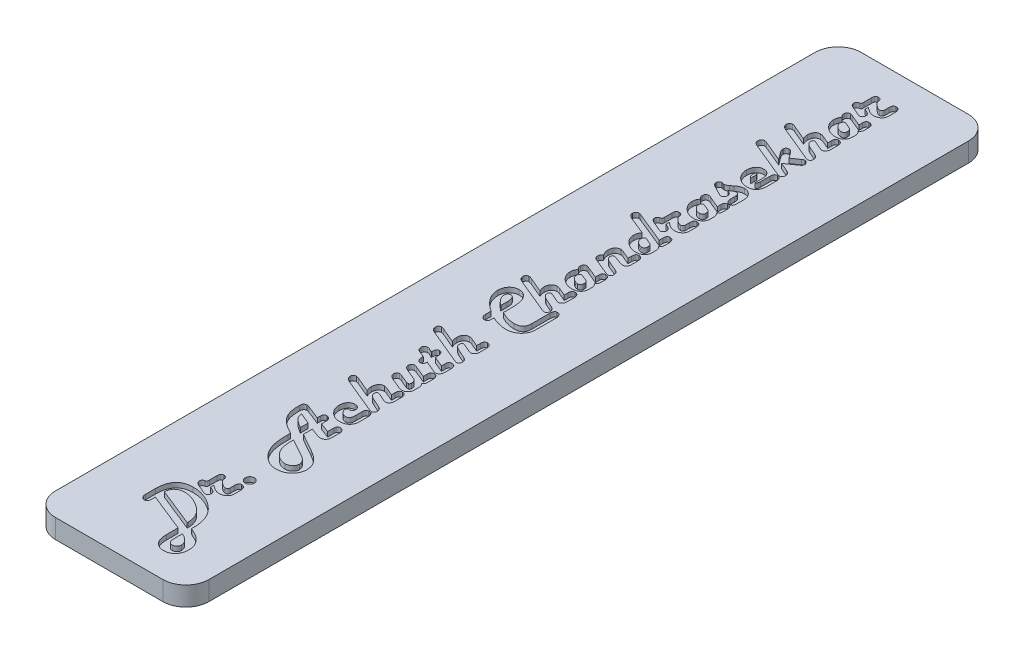
from build123d import *

# Parameters (mm, degrees)
BOSS_EXTRUDE1_DEPTH      = 66.675
BOSS_EXTRUDE1_DEPTH_BACK = 66.675
SKETCH3_W                = 25.4
SKETCH3_H                = 3.175
SKETCH5_OUTSIDE_W        = 54.556
SKETCH5_OUTSIDE_H        = 162.506
CUT_EXTRUDE2_DEPTH       = 68.947967225
CUT_EXTRUDE1_DEPTH       = 0.79375


with BuildPart() as part:
    # Sketch3 → Boss-Extrude1 (new, two sides: drawn at the far end of the back side and taken through both)
    with BuildSketch(Plane.XY.offset(-BOSS_EXTRUDE1_DEPTH_BACK)):
        Rectangle(SKETCH3_W, SKETCH3_H)
    extrude(amount=BOSS_EXTRUDE1_DEPTH + BOSS_EXTRUDE1_DEPTH_BACK)

    # Sketch5 outside → Cut-Extrude2 (cut, through all)
    with BuildSketch(Plane(origin=(0, 1.5875, 0), x_dir=(1, 0, 0), z_dir=(0, 1, 0))):
        Rectangle(SKETCH5_OUTSIDE_W, SKETCH5_OUTSIDE_H)
        with BuildLine():
            Line((12.7, -62.865), (12.7, 62.865))
            ThreePointArc((12.7, 62.865), (11.584076836, 65.559076836), (8.89, 66.675))
            Line((8.89, 66.675), (-8.89, 66.675))
            ThreePointArc((-8.89, 66.675), (-11.584076836, 65.559076836), (-12.7, 62.865))
            Line((-12.7, 62.865), (-12.7, -62.865))
            ThreePointArc((-12.7, -62.865), (-11.584076836, -65.559076836), (-8.89, -66.675))
            Line((-8.89, -66.675), (8.89, -66.675))
            ThreePointArc((8.89, -66.675), (11.584076836, -65.559076836), (12.7, -62.865))
        make_face(mode=Mode.SUBTRACT)
    extrude(amount=-CUT_EXTRUDE2_DEPTH, mode=Mode.SUBTRACT)

    # Sketch4 → Cut-Extrude1 (cut)
    # profile 1 of 22: a face of its own
    with BuildSketch(Plane(origin=(0, 1.5875, 0), x_dir=(1, 0, 0), z_dir=(0, 1, 0))):
        with BuildLine():
            Line((-3.545643193, -55.490289265), (-3.545643193, -56.019613438))
            Line((-3.545643193, -56.019613438), (-3.545643193, -56.163830504))
            add(Edge.make_bspline(
                [(-3.545643193, -56.163830504), (-3.547095122, -56.213576338), (-3.549814938, -56.306762421), (-3.571370094, -56.437235062), (-3.608826542, -56.548859388), (-3.662912082, -56.641124734), (-3.732855113, -56.714329898), (-3.820481404, -56.764088907), (-3.922353573, -56.795061933), (-3.995487767, -56.797867947), (-4.033762491, -56.799336473)],
                knots=[0, 0, 0, 0, 1.305737749, 2.445965353, 3.459324035, 4.379959175, 5.233349143, 6.085046436, 6.997810513, 8, 8, 8, 8], degree=3))
            add(Edge.make_bspline(
                [(-4.033762491, -56.799336473), (-4.083785842, -56.796362941), (-4.18250788, -56.79049462), (-4.32412961, -56.741235954), (-4.449814879, -56.657022698), (-4.560360012, -56.546144209), (-4.649813495, -56.411631213), (-4.715652297, -56.259870183), (-4.756357971, -56.09357208), (-4.760599554, -55.977586664), (-4.762771832, -55.918186052)],
                knots=[0, 0, 0, 0, 0.941902933, 1.858863449, 2.78744378, 3.773831386, 4.79357467, 5.815409039, 6.881186575, 8, 8, 8, 8], degree=3))
            Line((-4.762771832, -55.918186052), (-4.762771832, -55.773968987))
            Line((-4.762771832, -55.773968987), (-4.762771832, -54.206598904))
            add(Edge.make_bspline(
                [(-4.762771832, -54.206598904), (-4.760892536, -54.0776185), (-4.757242081, -53.827079495), (-4.721905802, -53.463158676), (-4.663978736, -53.122312862), (-4.581880253, -52.804645738), (-4.476941321, -52.5097399), (-4.35108176, -52.236481481), (-4.197764362, -51.988391716), (-4.02271335, -51.763280672), (-3.825906259, -51.562669362), (-3.607147739, -51.388662674), (-3.367623492, -51.241829492), (-3.107028426, -51.123025764), (-2.82667889, -51.02900974), (-2.525932194, -50.963469639), (-2.204960839, -50.922836324), (-1.98421096, -50.918685876), (-1.870506512, -50.916548052)],
                knots=[0, 0, 0, 0, 1.240121913, 2.408884614, 3.512215636, 4.562072732, 5.559962685, 6.519078054, 7.449661058, 8.358196616, 9.256317547, 10.145746268, 11.039719344, 11.951275398, 12.894325228, 13.877939151, 14.906963136, 16, 16, 16, 16], degree=3))
            add(Edge.make_bspline(
                [(-1.870506512, -50.916548052), (-1.694362012, -50.920588864), (-1.344435653, -50.928616287), (-0.825373527, -51.000002655), (-0.317171078, -51.111613745), (0.179538721, -51.269898348), (0.665164638, -51.471608729), (1.138047125, -51.721057214), (1.602328555, -52.012072062), (1.894201001, -52.238842736), (2.042371885, -52.353964296)],
                knots=[0, 0, 0, 0, 0.99369571, 1.974062893, 2.951324249, 3.9272385, 4.912259598, 5.915104549, 6.941589699, 8, 8, 8, 8], degree=3))
            add(Edge.make_bspline(
                [(2.042371885, -52.353964296), (2.124030078, -52.42168881), (2.285377964, -52.555505231), (2.509952772, -52.770240063), (2.717606797, -52.99049513), (2.909752662, -53.216599402), (3.083002068, -53.450644653), (3.240966926, -53.690411817), (3.380859519, -53.937314713), (3.505064965, -54.191743187), (3.613396114, -54.455800926), (3.705080829, -54.732026154), (3.784286381, -55.020234399), (3.849706437, -55.321684204), (3.89729731, -55.635751232), (3.934991432, -55.961786381), (3.954667929, -56.30093768), (3.958190969, -56.531483629), (3.959983412, -56.648780196)],
                knots=[0, 0, 0, 0, 1.041972891, 2.058827374, 3.050103684, 4.014970579, 4.971989252, 5.909071109, 6.834104011, 7.757898592, 8.688895906, 9.635856426, 10.615406742, 11.624176682, 12.664286734, 13.734882699, 14.847559518, 16, 16, 16, 16], degree=3))
            Line((3.959983412, -56.648780196), (3.959983412, -57.025963289))
            Line((3.959983412, -57.025963289), (4.112124492, -57.090940209))
            add(Edge.make_bspline(
                [(4.112124492, -57.090940209), (4.180256086, -57.121610024), (4.311336134, -57.180616434), (4.500830041, -57.265324747), (4.67275276, -57.348457446), (4.830141077, -57.424049156), (4.971340894, -57.49515412), (5.096061113, -57.56210846), (5.206537562, -57.621486877), (5.331434643, -57.698267755), (5.476511474, -57.797597253), (5.645419622, -57.927471547), (5.81024758, -58.075175975), (5.914702309, -58.183261169), (5.967928705, -58.238337519)],
                knots=[0, 0, 0, 0, 1.222800361, 2.352575644, 3.396669397, 4.347862466, 5.210067408, 5.983579217, 6.664594993, 7.262130753, 8.381971782, 9.540587582, 10.746771362, 12, 12, 12, 12], degree=3))
            add(Edge.make_bspline(
                [(5.967928705, -58.238337519), (6.034228206, -58.313317012), (6.164747273, -58.460923758), (6.335244326, -58.69827639), (6.477584846, -58.944688608), (6.596901489, -59.197983948), (6.686914711, -59.460787504), (6.752023277, -59.73186825), (6.793160057, -60.010999742), (6.797676702, -60.200182959), (6.799950235, -60.295411703)],
                knots=[0, 0, 0, 0, 1.055914228, 2.078702545, 3.078046045, 4.055880218, 5.029205391, 6.004237832, 6.995397536, 8, 8, 8, 8], degree=3))
            add(Edge.make_bspline(
                [(6.799950235, -60.295411703), (6.797874071, -60.373122906), (6.793795372, -60.525789386), (6.769185135, -60.74929656), (6.724133405, -60.961831637), (6.662332417, -61.164016095), (6.583160855, -61.35633938), (6.486042299, -61.537948392), (6.371342792, -61.708384123), (6.239980779, -61.866391595), (6.09518379, -62.009824535), (5.939924509, -62.13571813), (5.774313724, -62.241347116), (5.600110861, -62.329452353), (5.414390175, -62.395269381), (5.220524879, -62.445335905), (5.016314433, -62.473925204), (4.87714218, -62.477466633), (4.806268168, -62.47927012)],
                knots=[0, 0, 0, 0, 1.126201464, 2.212463691, 3.25287726, 4.269850786, 5.272053028, 6.261782411, 7.249022054, 8.243830034, 9.23438794, 10.19795826, 11.134388982, 12.075812372, 13.02018767, 13.98375799, 14.973220915, 16, 16, 16, 16], degree=3))
            add(Edge.make_bspline(
                [(4.806268168, -62.47927012), (4.718287977, -62.476647616), (4.543984716, -62.471452003), (4.288421744, -62.416846038), (4.039828159, -62.337166582), (3.803954979, -62.220899928), (3.584029627, -62.077872018), (3.388088864, -61.908814626), (3.216083992, -61.716566068), (3.124914149, -61.571566255), (3.078832991, -61.498277115)],
                knots=[0, 0, 0, 0, 1.014242392, 2.009381349, 3.004557683, 4.021967388, 5.035219112, 6.025505851, 7.00200576, 8, 8, 8, 8], degree=3))
            add(Edge.make_bspline(
                [(3.078832991, -61.498277115), (3.051469429, -61.447494911), (2.995655247, -61.343913105), (2.928281919, -61.176347571), (2.871671662, -60.996514697), (2.823532763, -60.804021847), (2.788369641, -60.598344781), (2.760901856, -60.380023527), (2.745122068, -60.148788916), (2.743623323, -59.990096593), (2.742854773, -59.908719792)],
                knots=[0, 0, 0, 0, 0.84245226, 1.718372183, 2.633912599, 3.596293803, 4.615457363, 5.681185209, 6.810920853, 8, 8, 8, 8], degree=3))
            Line((2.742854773, -59.908719792), (2.742854773, -58.0101259))
            Line((2.742854773, -58.0101259), (-3.545643193, -55.490289265))
        make_face()
        with BuildLine():
            Line((2.742854773, -56.506147933), (2.742854773, -56.29219954))
            add(Edge.make_bspline(
                [(2.742854773, -56.29219954), (2.741564504, -56.223484728), (2.73900962, -56.087421372), (2.720777645, -55.885337701), (2.693113113, -55.687190755), (2.651335537, -55.493636765), (2.599041168, -55.304702804), (2.535685004, -55.119681026), (2.458782651, -54.939202869), (2.372804564, -54.761433954), (2.271321113, -54.589991769), (2.160982187, -54.421758778), (2.037828763, -54.25847038), (1.905801368, -54.097598735), (1.757738715, -53.944490994), (1.602367504, -53.791440921), (1.431567674, -53.646046892), (1.312133723, -53.553206102), (1.25155523, -53.506116015)],
                knots=[0, 0, 0, 0, 1.003752549, 1.98754731, 2.96218803, 3.924869515, 4.877913061, 5.824875223, 6.779479857, 7.742439712, 8.707376773, 9.687714611, 10.680189018, 11.694008127, 12.725763052, 13.790025714, 14.879071578, 16, 16, 16, 16], degree=3))
            add(Edge.make_bspline(
                [(1.25155523, -53.506116015), (1.131347813, -53.418610403), (0.891548166, -53.244047008), (0.509374144, -53.017113473), (0.113728068, -52.815979049), (-0.293005766, -52.647151811), (-0.698348837, -52.509657913), (-1.0935029, -52.410276613), (-1.473371327, -52.348027376), (-1.722374844, -52.340294873), (-1.843564863, -52.336531464)],
                knots=[0, 0, 0, 0, 1.061151743, 2.116872814, 3.169496409, 4.227969904, 5.258553914, 6.222792805, 7.135033211, 8, 8, 8, 8], degree=3))
            add(Edge.make_bspline(
                [(-1.843564863, -52.336531464), (-1.907546183, -52.337563086), (-2.032690083, -52.339580881), (-2.215572414, -52.360786683), (-2.388228792, -52.394633666), (-2.549706304, -52.444752857), (-2.701391617, -52.506293937), (-2.843078983, -52.582341723), (-2.973283601, -52.67339997), (-3.093039417, -52.776296243), (-3.198539234, -52.892743993), (-3.293638645, -53.017734278), (-3.370569858, -53.154972739), (-3.434532919, -53.300986869), (-3.486209003, -53.456680331), (-3.519074615, -53.623403336), (-3.543273273, -53.799129446), (-3.544839068, -53.91965836), (-3.545643193, -53.98155689)],
                knots=[0, 0, 0, 0, 1.145531499, 2.240595844, 3.292755274, 4.292422607, 5.264114043, 6.220902991, 7.165828125, 8.104908158, 9.042461542, 9.975419986, 10.911970153, 11.852526766, 12.827988561, 13.843075609, 14.892295267, 16, 16, 16, 16], degree=3))
            Line((-3.545643193, -53.98155689), (2.742854773, -56.506147933))
        make_face(mode=Mode.SUBTRACT)
        with BuildLine():
            Line((3.959983412, -58.528356453), (3.959983412, -59.946755062))
            add(Edge.make_bspline(
                [(3.959983412, -59.946755062), (3.962342826, -60.026141475), (3.966757713, -60.174687639), (4.000727162, -60.382566457), (4.058970884, -60.560104477), (4.146616927, -60.704958881), (4.256543008, -60.821085885), (4.394499787, -60.901442401), (4.55583368, -60.950145626), (4.671192907, -60.955203042), (4.731782431, -60.957859321)],
                knots=[0, 0, 0, 0, 1.31364871, 2.458071474, 3.475829816, 4.38621616, 5.23967168, 6.094559773, 6.99921559, 8, 8, 8, 8], degree=3))
            add(Edge.make_bspline(
                [(4.731782431, -60.957859321), (4.782846729, -60.955334887), (4.882659896, -60.950400483), (5.024860797, -60.905133376), (5.155483977, -60.834591924), (5.26723375, -60.733702049), (5.363359665, -60.616119222), (5.432244359, -60.481105416), (5.473042101, -60.333144301), (5.478562347, -60.230693247), (5.48139421, -60.178136287)],
                knots=[0, 0, 0, 0, 1.015443884, 1.984844108, 2.946375274, 3.953924431, 4.965428653, 5.959234333, 6.953095811, 8, 8, 8, 8], degree=3))
            add(Edge.make_bspline(
                [(5.48139421, -60.178136287), (5.480166652, -60.137918251), (5.477713976, -60.05756211), (5.458073682, -59.937952817), (5.425372008, -59.820080121), (5.383729007, -59.702370849), (5.325403641, -59.587763022), (5.254608814, -59.475318468), (5.174712015, -59.361808744), (5.044589977, -59.21524988), (4.858094199, -59.037161958), (4.595525881, -58.845704902), (4.29431364, -58.671696197), (4.07414428, -58.577301443), (3.959983412, -58.528356453)],
                knots=[0, 0, 0, 0, 0.609246736, 1.21728261, 1.830931323, 2.461525313, 3.105941494, 3.774613737, 4.474427454, 5.206422339, 6.740961797, 8.372497183, 10.119089455, 12, 12, 12, 12], degree=3))
        make_face(mode=Mode.SUBTRACT)
    # profile 2 of 22: a face of its own
    with BuildSketch(Plane(origin=(0, 1.5875, 0), x_dir=(1, 0, 0), z_dir=(0, 1, 0))):
        with BuildLine():
            Line((-0.40139421, -49.482301414), (0.032841789, -49.670892961))
            add(Edge.make_bspline(
                [(0.032841789, -49.670892961), (0.078760205, -49.692156674), (0.166231274, -49.73266242), (0.283819488, -49.805019092), (0.385761084, -49.879059427), (0.468796341, -49.959947364), (0.533883304, -50.046263639), (0.578799843, -50.13836534), (0.60723926, -50.234995312), (0.610990336, -50.301452588), (0.612879655, -50.334925382)],
                knots=[0, 0, 0, 0, 1.297501196, 2.471640463, 3.537215363, 4.524637192, 5.43567625, 6.296618738, 7.14205136, 8, 8, 8, 8], degree=3))
            add(Edge.make_bspline(
                [(0.612879655, -50.334925382), (0.611761943, -50.374736217), (0.609587532, -50.452184724), (0.581108516, -50.562281771), (0.538568721, -50.663611655), (0.476541403, -50.750572542), (0.404440042, -50.824831183), (0.320597586, -50.878617942), (0.227227608, -50.909745031), (0.162492806, -50.914252036), (0.129514766, -50.916548052)],
                knots=[0, 0, 0, 0, 1.131994738, 2.202197021, 3.220602635, 4.248319073, 5.22801886, 6.155513921, 7.060358075, 8, 8, 8, 8], degree=3))
            add(Edge.make_bspline(
                [(0.129514766, -50.916548052), (0.106179514, -50.914480885), (0.051915089, -50.909673837), (-0.038309142, -50.885533802), (-0.148248779, -50.846202392), (-0.227722894, -50.813881985), (-0.271440371, -50.796103031)],
                knots=[0, 0, 0, 0, 0.667539348, 1.552314029, 2.65356594, 4, 4, 4, 4], degree=3))
            Line((-0.271440371, -50.796103031), (-1.707271812, -50.179614697))
            add(Edge.make_bspline(
                [(-1.707271812, -50.179614697), (-1.748446096, -50.161021729), (-1.827068906, -50.125518227), (-1.932826299, -50.059144411), (-2.023581417, -49.988844853), (-2.098044964, -49.911648722), (-2.156279888, -49.829062897), (-2.195962734, -49.739489976), (-2.223314567, -49.645034145), (-2.225815773, -49.579172076), (-2.227087168, -49.545693531)],
                knots=[0, 0, 0, 0, 1.242093141, 2.371792344, 3.427691145, 4.394328043, 5.313892613, 6.192305435, 7.081125362, 8, 8, 8, 8], degree=3))
            add(Edge.make_bspline(
                [(-2.227087168, -49.545693531), (-2.225720852, -49.513408256), (-2.223127082, -49.452118932), (-2.207661488, -49.364215637), (-2.179405162, -49.286287139), (-2.13892172, -49.218149288), (-2.08723593, -49.159375617), (-2.02280609, -49.112496369), (-1.948354435, -49.072861774), (-1.893082509, -49.056582059), (-1.864167301, -49.048065415)],
                knots=[0, 0, 0, 0, 1.15314347, 2.189090296, 3.173792814, 4.095790583, 5.004376053, 5.947550008, 6.926271946, 8, 8, 8, 8], degree=3))
            Line((-1.864167301, -49.048065415), (-1.704102206, -49.003690934))
            add(Edge.make_bspline(
                [(-1.704102206, -49.003690934), (-1.684845254, -48.998556305), (-1.649573718, -48.989151586), (-1.603832882, -48.966587265), (-1.569345468, -48.940157706), (-1.544863416, -48.904499118), (-1.531890203, -48.854376177), (-1.523531625, -48.784749024), (-1.517260875, -48.692105288), (-1.517154328, -48.622290113), (-1.517095462, -48.583718161)],
                knots=[0, 0, 0, 0, 0.926850573, 1.697643703, 2.362895762, 2.92973869, 3.677374781, 4.746381598, 6.202419277, 8, 8, 8, 8], degree=3))
            Line((-1.517095462, -48.583718161), (-1.517095462, -47.331723859))
            add(Edge.make_bspline(
                [(-1.517095462, -47.331723859), (-1.515702056, -47.278803504), (-1.51309606, -47.179830073), (-1.490897645, -47.041287283), (-1.45572989, -46.923126262), (-1.405383171, -46.824482086), (-1.336597151, -46.748945251), (-1.253085283, -46.695084736), (-1.154889049, -46.662439126), (-1.084703322, -46.658603815), (-1.047993799, -46.656597817)],
                knots=[0, 0, 0, 0, 1.361355543, 2.546053047, 3.599677592, 4.524244374, 5.371169927, 6.197098625, 7.057021238, 8, 8, 8, 8], degree=3))
            add(Edge.make_bspline(
                [(-1.047993799, -46.656597817), (-0.996918167, -46.658396327), (-0.89972732, -46.661818678), (-0.76493708, -46.704879946), (-0.648793438, -46.772250058), (-0.557366278, -46.87174018), (-0.484299221, -46.995619634), (-0.435552078, -47.147009121), (-0.405367977, -47.324176192), (-0.402778246, -47.450968616), (-0.40139421, -47.518730603)],
                knots=[0, 0, 0, 0, 0.994284648, 1.892005291, 2.734571892, 3.588753721, 4.500369607, 5.525254763, 6.677415825, 8, 8, 8, 8], degree=3))
            Line((-0.40139421, -47.518730603), (-0.349095714, -47.574198705))
            add(Edge.make_bspline(
                [(-0.349095714, -47.574198705), (-0.285176378, -47.637611467), (-0.16282523, -47.758992957), (0.019831512, -47.923377592), (0.19204532, -48.062126712), (0.350924397, -48.177742831), (0.501002302, -48.265790467), (0.638463394, -48.33006029), (0.765728988, -48.372380571), (0.848218934, -48.378148277), (0.88705056, -48.380863388)],
                knots=[0, 0, 0, 0, 1.435762249, 2.748263184, 3.91660617, 4.961556361, 5.879059361, 6.685751502, 7.381325737, 8, 8, 8, 8], degree=3))
            add(Edge.make_bspline(
                [(0.88705056, -48.380863388), (0.921061715, -48.380191223), (0.98568879, -48.378913991), (1.074975133, -48.354768624), (1.154008017, -48.323808703), (1.215589806, -48.271680707), (1.265275827, -48.207861391), (1.299057202, -48.129345022), (1.320462123, -48.037563397), (1.322031745, -47.972123452), (1.322871361, -47.937118572)],
                knots=[0, 0, 0, 0, 1.140484469, 2.167117703, 3.098941929, 3.971150526, 4.846255631, 5.80154673, 6.824011975, 8, 8, 8, 8], degree=3))
            Line((1.322871361, -47.937118572), (1.322871361, -47.26199253))
            add(Edge.make_bspline(
                [(1.322871361, -47.26199253), (1.32436563, -47.206463624), (1.327154637, -47.102820619), (1.348029178, -46.957310029), (1.387551487, -46.834263049), (1.440588385, -46.731712211), (1.511348593, -46.651961489), (1.597962563, -46.594781614), (1.701330995, -46.560594234), (1.775327838, -46.55703714), (1.814160265, -46.55517043)],
                knots=[0, 0, 0, 0, 1.364190584, 2.546219988, 3.596843527, 4.525897283, 5.362221888, 6.186477391, 7.048290713, 8, 8, 8, 8], degree=3))
            add(Edge.make_bspline(
                [(1.814160265, -46.55517043), (1.868932408, -46.55803936), (1.974255616, -46.563556123), (2.122212641, -46.610711141), (2.250708756, -46.688997645), (2.355653059, -46.799978936), (2.441175687, -46.936390847), (2.497793885, -47.100045623), (2.535546082, -47.285621889), (2.538464933, -47.417616572), (2.54, -47.487034544)],
                knots=[0, 0, 0, 0, 0.982615473, 1.889504555, 2.759142238, 3.658944971, 4.610088785, 5.631441668, 6.75433984, 8, 8, 8, 8], degree=3))
            Line((2.54, -47.487034544), (2.54, -48.536174074))
            add(Edge.make_bspline(
                [(2.54, -48.536174074), (2.538743063, -48.577976174), (2.536281608, -48.659837066), (2.518072169, -48.779744925), (2.490368348, -48.894369193), (2.448574191, -49.002612738), (2.395563619, -49.104879165), (2.332355573, -49.202399429), (2.255464351, -49.292595914), (2.168468565, -49.376570658), (2.072015732, -49.451948853), (1.969049153, -49.519164588), (1.858271574, -49.574793527), (1.741185011, -49.620960604), (1.616245445, -49.655672535), (1.484770355, -49.680562684), (1.346541434, -49.6972691), (1.25213374, -49.698693402), (1.204011143, -49.699419414)],
                knots=[0, 0, 0, 0, 1.009407673, 1.976719137, 2.923785669, 3.852797958, 4.771676065, 5.702527031, 6.65345443, 7.628144937, 8.618662201, 9.606215811, 10.593522047, 11.607757909, 12.641947342, 13.720607507, 14.838121302, 16, 16, 16, 16], degree=3))
            add(Edge.make_bspline(
                [(1.204011143, -49.699419414), (1.141541464, -49.697171755), (1.01634334, -49.692667128), (0.830349738, -49.659587775), (0.646694301, -49.607535827), (0.4630088, -49.530335038), (0.271762343, -49.424978101), (0.064369716, -49.288924148), (-0.163448457, -49.120301793), (-0.319009463, -48.993297022), (-0.40139421, -48.926035591)],
                knots=[0, 0, 0, 0, 0.822710096, 1.64882809, 2.481516469, 3.333299355, 4.267584386, 5.354441073, 6.598918144, 8, 8, 8, 8], degree=3))
            Line((-0.40139421, -48.926035591), (-0.40139421, -49.482301414))
        make_face()
    # profile 3 of 22: a face of its own
    with BuildSketch(Plane(origin=(0, 1.5875, 0), x_dir=(1, 0, 0), z_dir=(0, 1, 0))):
        with BuildLine():
            add(Edge.make_bspline(
                [(1.120016588, -45.284158492), (1.122686775, -45.233662941), (1.127897779, -45.13511836), (1.171288982, -44.993093284), (1.242213155, -44.862462942), (1.340628947, -44.747235058), (1.455856831, -44.648819266), (1.586487174, -44.577895093), (1.728512249, -44.53450389), (1.82705683, -44.529292886), (1.877552382, -44.526622699)],
                knots=[0, 0, 0, 0, 1.018015329, 1.986707578, 2.970091954, 4, 5.029908046, 6.013292422, 6.981984671, 8, 8, 8, 8], degree=3))
            add(Edge.make_bspline(
                [(1.877552382, -44.526622699), (1.928559168, -44.529352545), (2.028614938, -44.534707457), (2.172850993, -44.577567071), (2.305332157, -44.648357612), (2.42078765, -44.747278135), (2.519237787, -44.862451979), (2.590153205, -44.993096098), (2.633546667, -45.135117619), (2.638757359, -45.23366269), (2.641427387, -45.284158492)],
                knots=[0, 0, 0, 0, 1.023458974, 2.007634331, 2.995409192, 4.02013336, 5.044857529, 6.023292197, 6.987108688, 8, 8, 8, 8], degree=3))
            add(Edge.make_bspline(
                [(2.641427387, -45.284158492), (2.638697703, -45.335165534), (2.633343109, -45.435221804), (2.590481178, -45.579454214), (2.519699507, -45.711949338), (2.4207446, -45.827350711), (2.305343227, -45.926305617), (2.172848103, -45.997087289), (2.028615693, -46.039949219), (1.928559423, -46.045303813), (1.877552382, -46.048033497)],
                knots=[0, 0, 0, 0, 1.018333356, 1.997579833, 2.980407786, 4, 5.019592214, 6.002420167, 6.981666644, 8, 8, 8, 8], degree=3))
            add(Edge.make_bspline(
                [(1.877552382, -46.048033497), (1.827056579, -46.04536347), (1.728511508, -46.040152778), (1.586489987, -45.996759315), (1.455845868, -45.925843898), (1.340672024, -45.827393761), (1.241751501, -45.711938268), (1.17096096, -45.579457104), (1.128101346, -45.435221049), (1.122746434, -45.335165279), (1.120016588, -45.284158492)],
                knots=[0, 0, 0, 0, 1.012891312, 1.976707803, 2.955142471, 3.97986664, 5.004590808, 5.992365669, 6.976541026, 8, 8, 8, 8], degree=3))
        make_face()
    # profile 4 of 22: a face of its own
    with BuildSketch(Plane(origin=(0, 1.5875, 0), x_dir=(1, 0, 0), z_dir=(0, 1, 0))):
        with BuildLine():
            Line((-0.299966824, -32.754706647), (-0.299966824, -34.236497372))
            Line((-0.299966824, -34.236497372), (2.842697357, -36.01306144))
            add(Edge.make_bspline(
                [(2.842697357, -36.01306144), (2.933596562, -36.064958143), (3.11142719, -36.166486239), (3.363354717, -36.331469925), (3.59980505, -36.496388239), (3.817437538, -36.667193217), (4.01956236, -36.839360093), (4.20353896, -37.016407118), (4.368577143, -37.198382744), (4.51915124, -37.381358403), (4.64842296, -37.571346975), (4.763955372, -37.762359846), (4.858853354, -37.959201861), (4.939272567, -38.158274057), (4.998589428, -38.362491788), (5.044239581, -38.568724637), (5.06943129, -38.779506004), (5.073589004, -38.921114397), (5.075684664, -38.99249092)],
                knots=[0, 0, 0, 0, 1.284127512, 2.512202389, 3.693820525, 4.820683154, 5.905595552, 6.95085666, 7.951169987, 8.919030195, 9.855848477, 10.768583501, 11.655730142, 12.534476643, 13.400021201, 14.262063092, 15.124007484, 16, 16, 16, 16], degree=3))
            add(Edge.make_bspline(
                [(5.075684664, -38.99249092), (5.073089975, -39.07924176), (5.068005704, -39.249229259), (5.032573735, -39.499518749), (4.972750573, -39.73866533), (4.887598482, -39.967382399), (4.780235703, -40.185290521), (4.646134181, -40.391235035), (4.491513364, -40.588305018), (4.312196333, -40.770538625), (4.117284973, -40.938067223), (3.907836255, -41.084683824), (3.685888549, -41.206091612), (3.45474663, -41.310195269), (3.20993779, -41.385793022), (2.955384919, -41.444169119), (2.688806421, -41.477607316), (2.507337835, -41.481709336), (2.41480057, -41.483801102)],
                knots=[0, 0, 0, 0, 1.023509052, 2.005556865, 2.976162568, 3.926806602, 4.88020563, 5.83639235, 6.821600422, 7.8310613, 8.847943164, 9.850897116, 10.841415261, 11.829399931, 12.83678008, 13.859073563, 14.908265711, 16, 16, 16, 16], degree=3))
            add(Edge.make_bspline(
                [(2.41480057, -41.483801102), (2.338638217, -41.482574068), (2.186355711, -41.48012068), (1.959322731, -41.450963714), (1.733933188, -41.409284985), (1.510643915, -41.347830122), (1.289370094, -41.271068108), (1.070755149, -41.17424956), (0.853820151, -41.062288839), (0.64091175, -40.932361021), (0.433702445, -40.788132178), (0.233206291, -40.631563275), (0.043751197, -40.459892689), (-0.137759176, -40.276892495), (-0.310704719, -40.082013713), (-0.473989336, -39.873893529), (-0.628315733, -39.653121869), (-0.722847555, -39.498554199), (-0.770653289, -39.420387707)],
                knots=[0, 0, 0, 0, 0.920360802, 1.840211654, 2.763493683, 3.690106123, 4.637553702, 5.592892168, 6.578521632, 7.587450506, 8.606298991, 9.629842057, 10.661069622, 11.695398393, 12.745173504, 13.809615302, 14.892299487, 16, 16, 16, 16], degree=3))
            add(Edge.make_bspline(
                [(-0.770653289, -39.420387707), (-0.836233704, -39.29889984), (-0.968117731, -39.054584377), (-1.127296245, -38.665758072), (-1.255289573, -38.258254243), (-1.338724753, -37.903606573), (-1.391284116, -37.603860125), (-1.423148935, -37.358837429), (-1.454901596, -37.096533292), (-1.474808253, -36.815601256), (-1.49530617, -36.51724767), (-1.506800556, -36.200665131), (-1.51510633, -35.866247431), (-1.516421335, -35.637469123), (-1.517095462, -35.520187733)],
                knots=[0, 0, 0, 0, 1.235982978, 2.485595966, 3.756177378, 5.05891948, 5.745857238, 6.481327979, 7.271967052, 8.112145328, 9.003570026, 9.950725021, 10.949455392, 12, 12, 12, 12], degree=3))
            Line((-1.517095462, -35.520187733), (-1.517095462, -35.123987005))
            Line((-1.517095462, -35.123987005), (-2.284140073, -34.704014232))
            add(Edge.make_bspline(
                [(-2.284140073, -34.704014232), (-2.413081472, -34.630790439), (-2.66476605, -34.487862725), (-3.014874517, -34.248618896), (-3.334663687, -34.000460971), (-3.617677885, -33.736447318), (-3.871743537, -33.464005458), (-4.086529982, -33.174927948), (-4.274370735, -32.877033465), (-4.370930573, -32.666088472), (-4.4188696, -32.561360691)],
                knots=[0, 0, 0, 0, 1.154231185, 2.252978409, 3.298924017, 4.303170672, 5.263936639, 6.195269199, 7.104005978, 8, 8, 8, 8], degree=3))
            add(Edge.make_bspline(
                [(-4.4188696, -32.561360691), (-4.446814385, -32.491463169), (-4.504111213, -32.348148194), (-4.572818962, -32.120563557), (-4.630834076, -31.87749085), (-4.680589214, -31.619630557), (-4.715987119, -31.345356684), (-4.742407554, -31.056191812), (-4.761101313, -30.751229436), (-4.762205928, -30.542879456), (-4.762771832, -30.436139982)],
                knots=[0, 0, 0, 0, 0.833580457, 1.709138717, 2.630308376, 3.601286859, 4.616795241, 5.692327562, 6.817759698, 8, 8, 8, 8], degree=3))
            add(Edge.make_bspline(
                [(-4.762771832, -30.436139982), (-4.760972722, -30.383201576), (-4.757546381, -30.282382292), (-4.731298995, -30.139822131), (-4.685170494, -30.015006278), (-4.620107709, -29.908624662), (-4.53704533, -29.823783016), (-4.439073755, -29.76038418), (-4.324431067, -29.725612059), (-4.243706482, -29.720750798), (-4.2017516, -29.718224262)],
                knots=[0, 0, 0, 0, 1.235229773, 2.35245055, 3.366973227, 4.325000809, 5.240507286, 6.116206508, 7.020938506, 8, 8, 8, 8], degree=3))
            add(Edge.make_bspline(
                [(-4.2017516, -29.718224262), (-4.157558612, -29.721840852), (-4.059846649, -29.729837236), (-3.96722046, -29.762268347), (-3.916487076, -29.780031575)],
                knots=[0, 0, 0, 0, 0.904556353, 2, 2, 2, 2], degree=3))
            Line((-3.916487076, -29.780031575), (-3.796042054, -29.827575663))
            Line((-3.796042054, -29.827575663), (-1.517095462, -30.716650098))
            Line((-1.517095462, -30.716650098), (-1.517095462, -30.310940552))
            Line((-1.517095462, -30.310940552), (-1.517095462, -30.171477895))
            add(Edge.make_bspline(
                [(-1.517095462, -30.171477895), (-1.515820469, -30.128026414), (-1.513419242, -30.046193137), (-1.489403663, -29.932194788), (-1.451623101, -29.834296185), (-1.397587352, -29.752752286), (-1.324946324, -29.690274112), (-1.236802766, -29.648015547), (-1.134781083, -29.619599797), (-1.061417102, -29.617766143), (-1.022636953, -29.616796875)],
                knots=[0, 0, 0, 0, 1.224457869, 2.306052593, 3.269225765, 4.170438305, 5.03696607, 5.936821825, 6.909405468, 8, 8, 8, 8], degree=3))
            add(Edge.make_bspline(
                [(-1.022636953, -29.616796875), (-0.974182442, -29.619253367), (-0.878810182, -29.624088443), (-0.742565701, -29.671349552), (-0.617947995, -29.74582005), (-0.508630753, -29.847919493), (-0.414528801, -29.968303809), (-0.347904495, -30.106733076), (-0.306116336, -30.25780473), (-0.302057611, -30.36295558), (-0.299966824, -30.417122347)],
                knots=[0, 0, 0, 0, 0.967844388, 1.904993043, 2.854314898, 3.858179587, 4.884883616, 5.897857367, 6.917115065, 8, 8, 8, 8], degree=3))
            Line((-0.299966824, -30.417122347), (-0.299966824, -30.561339412))
            Line((-0.299966824, -30.561339412), (-0.299966824, -31.236465454))
            Line((-0.299966824, -31.236465454), (1.322871361, -31.829181744))
            Line((1.322871361, -31.829181744), (1.322871361, -30.957540141))
            Line((1.322871361, -30.957540141), (1.322871361, -30.818077485))
            add(Edge.make_bspline(
                [(1.322871361, -30.818077485), (1.324349001, -30.771505723), (1.327122167, -30.684102023), (1.348418415, -30.561840474), (1.386501997, -30.457820873), (1.440071563, -30.371631837), (1.511910102, -30.30585317), (1.597426101, -30.256691703), (1.700189699, -30.230677208), (1.772825098, -30.227192303), (1.810990659, -30.225361194)],
                knots=[0, 0, 0, 0, 1.273098158, 2.389290989, 3.376549181, 4.286045457, 5.134299476, 6.013945099, 6.956446832, 8, 8, 8, 8], degree=3))
            add(Edge.make_bspline(
                [(1.810990659, -30.225361194), (1.860527604, -30.228312772), (1.957628631, -30.234098377), (2.096180714, -30.283066529), (2.222969471, -30.360477133), (2.331378181, -30.469673697), (2.425647499, -30.596104594), (2.492422248, -30.741312812), (2.533642055, -30.899272252), (2.53784581, -31.009051154), (2.54, -31.065306739)],
                knots=[0, 0, 0, 0, 0.959970407, 1.881708946, 2.821665646, 3.823251842, 4.851715016, 5.871022397, 6.909017313, 8, 8, 8, 8], degree=3))
            Line((2.54, -31.065306739), (2.54, -31.209523805))
            Line((2.54, -31.209523805), (2.54, -32.353751509))
            add(Edge.make_bspline(
                [(2.54, -32.353751509), (2.537068286, -32.425322349), (2.531420789, -32.563192567), (2.485018926, -32.760111989), (2.406295365, -32.935897305), (2.298640063, -33.088869329), (2.165369311, -33.213398096), (2.010939098, -33.304604987), (1.837493106, -33.360840595), (1.715272756, -33.366634765), (1.652510368, -33.369610178)],
                knots=[0, 0, 0, 0, 1.135640793, 2.187637353, 3.190204587, 4.177136149, 5.13878535, 6.063917208, 7.005786023, 8, 8, 8, 8], degree=3))
            add(Edge.make_bspline(
                [(1.652510368, -33.369610178), (1.596351365, -33.366746644), (1.471810736, -33.360396348), (1.270956096, -33.316894214), (1.038551575, -33.249282434), (0.875110212, -33.190464776), (0.787207976, -33.15883139)],
                knots=[0, 0, 0, 0, 0.753316793, 1.670587834, 2.747192678, 4, 4, 4, 4], degree=3))
            Line((0.787207976, -33.15883139), (-0.299966824, -32.754706647))
        make_face()
        with BuildLine():
            Line((-1.517095462, -32.230136882), (-3.361806055, -31.459922665))
            add(Edge.make_bspline(
                [(-3.361806055, -31.459922665), (-3.353094538, -31.551277942), (-3.336129583, -31.729184752), (-3.262696511, -31.981838167), (-3.157074182, -32.212452371), (-3.039516834, -32.38791323), (-2.921890284, -32.518025646), (-2.819631893, -32.621124777), (-2.699163709, -32.725310672), (-2.56483626, -32.834772167), (-2.41396065, -32.947126355), (-2.246809696, -33.062383538), (-2.065492479, -33.183370753), (-1.936852852, -33.261281111), (-1.870506512, -33.301463652)],
                knots=[0, 0, 0, 0, 1.327479438, 2.585155888, 3.790872231, 4.992669277, 5.627155637, 6.330882107, 7.09570796, 7.933840435, 8.841788147, 9.820799051, 10.876069462, 12, 12, 12, 12], degree=3))
            Line((-1.870506512, -33.301463652), (-1.517095462, -33.520166455))
            Line((-1.517095462, -33.520166455), (-1.517095462, -32.230136882))
        make_face(mode=Mode.SUBTRACT)
        with BuildLine():
            Line((-0.299966824, -35.857750754), (-0.299966824, -36.311004388))
            add(Edge.make_bspline(
                [(-0.299966824, -36.311004388), (-0.29809306, -36.434140395), (-0.294437376, -36.674376857), (-0.267421968, -37.02525706), (-0.222379898, -37.356793695), (-0.156928009, -37.668477765), (-0.07569926, -37.960962993), (0.026361499, -38.233326167), (0.145824023, -38.486940912), (0.24216224, -38.643062067), (0.289579861, -38.719904819)],
                knots=[0, 0, 0, 0, 1.17507216, 2.292547767, 3.356328211, 4.36586142, 5.329840842, 6.250349605, 7.138822986, 8, 8, 8, 8], degree=3))
            add(Edge.make_bspline(
                [(0.289579861, -38.719904819), (0.354003417, -38.811413072), (0.481756384, -38.992875439), (0.709706705, -39.233339294), (0.958024932, -39.447960964), (1.227195685, -39.630201654), (1.508991093, -39.778418619), (1.797550786, -39.882877892), (2.087299339, -39.950783404), (2.28184507, -39.958541751), (2.378350103, -39.962390304)],
                knots=[0, 0, 0, 0, 1.061931571, 2.105827722, 3.137883091, 4.174868311, 5.187188109, 6.15404082, 7.084306037, 8, 8, 8, 8], degree=3))
            add(Edge.make_bspline(
                [(2.378350103, -39.962390304), (2.463227415, -39.958467975), (2.629408837, -39.950788441), (2.869037077, -39.889369182), (3.088331042, -39.785847999), (3.25233379, -39.667917508), (3.368572637, -39.557886003), (3.446038972, -39.470491385), (3.509410709, -39.377068889), (3.563799955, -39.281150059), (3.605737709, -39.180121342), (3.633827263, -39.074528437), (3.651805766, -38.965102406), (3.654395157, -38.890604946), (3.655701252, -38.853028263)],
                knots=[0, 0, 0, 0, 1.625345399, 3.182266278, 4.704124598, 6.249545861, 7.030225429, 7.76935358, 8.482720177, 9.189807842, 9.879872433, 10.572531956, 11.279981989, 12, 12, 12, 12], degree=3))
            add(Edge.make_bspline(
                [(3.655701252, -38.853028263), (3.652371495, -38.786651232), (3.645713672, -38.653930901), (3.590532163, -38.459067842), (3.501184144, -38.271734746), (3.379353982, -38.088881504), (3.219927035, -37.915059362), (3.027348275, -37.746058695), (2.80034239, -37.583159883), (2.632285579, -37.485496775), (2.544754409, -37.434629655)],
                knots=[0, 0, 0, 0, 0.841394824, 1.682362055, 2.549233927, 3.467926034, 4.460234473, 5.5338279, 6.715512172, 8, 8, 8, 8], degree=3))
            Line((2.544754409, -37.434629655), (-0.299966824, -35.857750754))
        make_face(mode=Mode.SUBTRACT)
    # profile 5 of 22: a face of its own
    with BuildSketch(Plane(origin=(0, 1.5875, 0), x_dir=(1, 0, 0), z_dir=(0, 1, 0))):
        with BuildLine():
            Line((2.54, -26.353687673), (2.54, -27.905209727))
            add(Edge.make_bspline(
                [(2.54, -27.905209727), (2.538224758, -27.959667655), (2.534747659, -28.066332341), (2.514925409, -28.222802953), (2.477001324, -28.370846041), (2.429521678, -28.512728972), (2.362696714, -28.645327507), (2.283992755, -28.770385158), (2.190486117, -28.887839289), (2.08360453, -28.996100426), (1.964834921, -29.093759797), (1.837768261, -29.18077623), (1.700065871, -29.251137229), (1.556018226, -29.312320184), (1.40246978, -29.358635569), (1.240292094, -29.388791453), (1.07043966, -29.411079375), (0.95421791, -29.412975542), (0.894974574, -29.413942102)],
                knots=[0, 0, 0, 0, 1.04308008, 2.043041565, 3.012085238, 3.965374515, 4.901770913, 5.84746328, 6.790555503, 7.770466118, 8.754752285, 9.731054025, 10.712842265, 11.710345077, 12.724731782, 13.776116382, 14.86638876, 16, 16, 16, 16], degree=3))
            add(Edge.make_bspline(
                [(0.894974574, -29.413942102), (0.815101657, -29.411738796), (0.65736301, -29.407387551), (0.424292641, -29.374867961), (0.199017934, -29.321474129), (-0.018188941, -29.244761448), (-0.226326764, -29.145598387), (-0.427401369, -29.026403376), (-0.61915225, -28.884154188), (-0.801731419, -28.724249405), (-0.968053192, -28.548391418), (-1.114400067, -28.362657679), (-1.239165246, -28.169838735), (-1.341813543, -27.969511015), (-1.419004428, -27.759995486), (-1.477086357, -27.543831384), (-1.51070781, -27.319361341), (-1.51495339, -27.167328143), (-1.517095462, -27.090621029)],
                knots=[0, 0, 0, 0, 1.032880778, 2.039805514, 3.03750717, 4.022966625, 5.013270403, 6.015198194, 7.041549148, 8.097010445, 9.150700833, 10.167706486, 11.151387667, 12.117033502, 13.072716193, 14.034000681, 15.008071015, 16, 16, 16, 16], degree=3))
            add(Edge.make_bspline(
                [(-1.517095462, -27.090621029), (-1.516386516, -27.038801431), (-1.515001232, -26.937545782), (-1.498253052, -26.789847027), (-1.473594404, -26.649193245), (-1.436885902, -26.516256113), (-1.391035991, -26.390496338), (-1.335180666, -26.271989062), (-1.268765603, -26.160667022), (-1.190934908, -26.058316884), (-1.106149335, -25.964765266), (-1.013693324, -25.883398068), (-0.914939824, -25.814416277), (-0.809506916, -25.759601726), (-0.699377877, -25.713168689), (-0.581539372, -25.684932311), (-0.458111729, -25.664284287), (-0.37349064, -25.662198735), (-0.330078079, -25.661128799)],
                knots=[0, 0, 0, 0, 1.192564817, 2.330275221, 3.41819661, 4.477524274, 5.501124758, 6.496810597, 7.48974376, 8.479841883, 9.452680265, 10.392095817, 11.309843112, 12.218518014, 13.12425749, 14.053539155, 15.001420906, 16, 16, 16, 16], degree=3))
            add(Edge.make_bspline(
                [(-0.330078079, -25.661128799), (-0.271186602, -25.663275094), (-0.157874294, -25.667404752), (0.003234144, -25.707106863), (0.149526944, -25.768509424), (0.275360279, -25.858104181), (0.381357622, -25.964678737), (0.457783183, -26.089923386), (0.504337024, -26.230040345), (0.509038515, -26.328496788), (0.511452269, -26.37904452)],
                knots=[0, 0, 0, 0, 1.140377676, 2.194185509, 3.199289063, 4.199942802, 5.170986714, 6.095385878, 7.022167372, 8, 8, 8, 8], degree=3))
            add(Edge.make_bspline(
                [(0.511452269, -26.37904452), (0.510459973, -26.418243057), (0.508595793, -26.491883527), (0.489219008, -26.594208351), (0.460273701, -26.682011164), (0.416278832, -26.753927786), (0.360278935, -26.811739824), (0.288657201, -26.849872092), (0.206660138, -26.87440452), (0.147670068, -26.87693485), (0.116836343, -26.878257438)],
                knots=[0, 0, 0, 0, 1.293872805, 2.430738727, 3.43019671, 4.33150824, 5.195698491, 6.055468302, 6.983605972, 8, 8, 8, 8], degree=3))
            add(Edge.make_bspline(
                [(0.116836343, -26.878257438), (0.098346976, -26.878257438), (0.064537847, -26.878257438), (0.030728718, -26.878257438), (0.015408956, -26.878257438)],
                knots=[0, 0, 0, 0, 1.09375, 2, 2, 2, 2], degree=3))
            add(Edge.make_bspline(
                [(0.015408956, -26.878257438), (-0.000439073, -26.878257438), (-0.032135131, -26.878257438), (-0.063831189, -26.878257438), (-0.079679218, -26.878257438)],
                knots=[0, 0, 0, 0, 1, 2, 2, 2, 2], degree=3))
            add(Edge.make_bspline(
                [(-0.079679218, -26.878257438), (-0.105168178, -26.879393029), (-0.153121056, -26.88152944), (-0.219889216, -26.899480603), (-0.277449536, -26.92761707), (-0.323401474, -26.971080359), (-0.358316678, -27.026328252), (-0.383361249, -27.092627378), (-0.399666109, -27.170141595), (-0.400792984, -27.225764037), (-0.40139421, -27.255440532)],
                knots=[0, 0, 0, 0, 1.076936836, 2.026062317, 2.906040588, 3.760364707, 4.665822401, 5.649858543, 6.746118299, 8, 8, 8, 8], degree=3))
            add(Edge.make_bspline(
                [(-0.40139421, -27.255440532), (-0.397578045, -27.314154713), (-0.389890745, -27.432428818), (-0.320983842, -27.602899813), (-0.213495311, -27.764112384), (-0.067849701, -27.910696156), (0.102855903, -28.034466212), (0.28744274, -28.129841627), (0.484531067, -28.185244892), (0.619417075, -28.192938059), (0.687365392, -28.196813463)],
                knots=[0, 0, 0, 0, 0.889763228, 1.792342931, 2.754811586, 3.822728083, 4.915314341, 5.949932207, 6.967286101, 8, 8, 8, 8], degree=3))
            add(Edge.make_bspline(
                [(0.687365392, -28.196813463), (0.741594374, -28.193993116), (0.843175892, -28.188710052), (0.984419567, -28.143712031), (1.099353712, -28.065688109), (1.187729784, -27.953184551), (1.250713196, -27.805407579), (1.292081829, -27.61924408), (1.318250801, -27.392993655), (1.321250528, -27.228584574), (1.322871361, -27.139749919)],
                knots=[0, 0, 0, 0, 0.921733385, 1.726587388, 2.489921751, 3.251187094, 4.128731787, 5.201937451, 6.488131425, 8, 8, 8, 8], degree=3))
            Line((1.322871361, -27.139749919), (1.322871361, -26.128645659))
            add(Edge.make_bspline(
                [(1.322871361, -26.128645659), (1.324105782, -26.076214488), (1.326427332, -25.977608289), (1.350787975, -25.840344807), (1.386420583, -25.721819304), (1.443972055, -25.626051794), (1.514119238, -25.548323562), (1.602876966, -25.4948722), (1.707079599, -25.464315557), (1.781189564, -25.460367945), (1.820499477, -25.458274026)],
                knots=[0, 0, 0, 0, 1.322412768, 2.487033816, 3.512186622, 4.427362607, 5.286259282, 6.130526476, 7.008381102, 8, 8, 8, 8], degree=3))
            add(Edge.make_bspline(
                [(1.820499477, -25.458274026), (1.873724239, -25.460468533), (1.976569777, -25.464708951), (2.12070557, -25.512927927), (2.247628367, -25.589172237), (2.352331239, -25.697884223), (2.435980022, -25.830983077), (2.499343531, -25.985526905), (2.53262436, -26.163175184), (2.537459118, -26.288056804), (2.54, -26.353687673)],
                knots=[0, 0, 0, 0, 0.983387488, 1.900187257, 2.783738441, 3.70487027, 4.669396318, 5.684275508, 6.782983353, 8, 8, 8, 8], degree=3))
        make_face()
    # profile 6 of 22: a face of its own
    with BuildSketch(Plane(origin=(0, 1.5875, 0), x_dir=(1, 0, 0), z_dir=(0, 1, 0))):
        with BuildLine():
            add(Edge.make_bspline(
                [(-1.293638251, -22.686453728), (-1.32781279, -22.597656322), (-1.392393188, -22.429853861), (-1.462110909, -22.185518537), (-1.506983101, -21.965415014), (-1.513873576, -21.826079902), (-1.517095462, -21.760928825)],
                knots=[0, 0, 0, 0, 1.192277109, 2.253072951, 3.183162251, 4, 4, 4, 4], degree=3))
            add(Edge.make_bspline(
                [(-1.517095462, -21.760928825), (-1.513938545, -21.678753754), (-1.507864019, -21.52063285), (-1.456164936, -21.295453325), (-1.371827945, -21.092673841), (-1.252613933, -20.917764932), (-1.109453233, -20.770876471), (-0.941238585, -20.666434356), (-0.754274632, -20.600282593), (-0.622772725, -20.593334167), (-0.555120093, -20.589759471)],
                knots=[0, 0, 0, 0, 1.163728747, 2.239241625, 3.256049629, 4.259308472, 5.223105438, 6.141580819, 7.043915403, 8, 8, 8, 8], degree=3))
            add(Edge.make_bspline(
                [(-0.555120093, -20.589759471), (-0.511705509, -20.591379186), (-0.422677354, -20.594700657), (-0.286540078, -20.619831937), (-0.145775131, -20.661466023), (-0.051932345, -20.698868415), (-0.003608679, -20.718128507)],
                knots=[0, 0, 0, 0, 0.913771887, 1.873827111, 2.905142604, 4, 4, 4, 4], degree=3))
            Line((-0.003608679, -20.718128507), (1.322871361, -21.280733542))
            Line((1.322871361, -21.280733542), (1.322871361, -20.665830011))
            add(Edge.make_bspline(
                [(1.322871361, -20.665830011), (1.324139658, -20.612358205), (1.326527571, -20.511682935), (1.350459029, -20.371620982), (1.386992977, -20.250996412), (1.442896454, -20.152507096), (1.51464114, -20.074570448), (1.602614889, -20.019453138), (1.706833486, -19.986816043), (1.781158502, -19.983140601), (1.820499477, -19.981195152)],
                knots=[0, 0, 0, 0, 1.332463939, 2.508727067, 3.533793541, 4.460473192, 5.308803215, 6.149629839, 7.020580579, 8, 8, 8, 8], degree=3))
            add(Edge.make_bspline(
                [(1.820499477, -19.981195152), (1.874238106, -19.983412763), (1.978088631, -19.987698322), (2.12347155, -20.03546283), (2.250814859, -20.112131059), (2.355706459, -20.221105692), (2.440351098, -20.355263513), (2.498232892, -20.515262643), (2.535467908, -20.697391612), (2.538437319, -20.827274384), (2.54, -20.895626434)],
                knots=[0, 0, 0, 0, 0.977613495, 1.889249429, 2.758984997, 3.665713581, 4.623297696, 5.633227242, 6.75446322, 8, 8, 8, 8], degree=3))
            Line((2.54, -20.895626434), (2.54, -21.97012281))
            add(Edge.make_bspline(
                [(2.54, -21.97012281), (2.538139747, -22.027898975), (2.534518983, -22.140353533), (2.498732602, -22.301337659), (2.441651043, -22.448683399), (2.361468056, -22.577122967), (2.265988695, -22.683966738), (2.1574107, -22.763134343), (2.036226984, -22.812195969), (1.950895125, -22.818147012), (1.907663637, -22.821161976)],
                knots=[0, 0, 0, 0, 1.178982844, 2.29475245, 3.351088271, 4.393433743, 5.371478754, 6.261126476, 7.119038396, 8, 8, 8, 8], degree=3))
            add(Edge.make_bspline(
                [(1.907663637, -22.821161976), (1.875318324, -22.819426781), (1.805656279, -22.815689696), (1.69657627, -22.789460003), (1.574592027, -22.751293659), (1.491113263, -22.71627052), (1.446485989, -22.697547348)],
                knots=[0, 0, 0, 0, 0.807812092, 1.739783524, 2.791701091, 4, 4, 4, 4], degree=3))
            Line((1.446485989, -22.697547348), (0.311767102, -22.203088839))
            add(Edge.make_bspline(
                [(0.311767102, -22.203088839), (0.278012852, -22.189776669), (0.215672502, -22.165190568), (0.128466809, -22.132601414), (0.052402332, -22.116849834), (0.005941251, -22.112917487), (-0.014702299, -22.11117027)],
                knots=[0, 0, 0, 0, 1.277520242, 2.359438044, 3.271066812, 4, 4, 4, 4], degree=3))
            add(Edge.make_bspline(
                [(-0.014702299, -22.11117027), (-0.037030483, -22.112281907), (-0.079944235, -22.114418425), (-0.140109656, -22.13367358), (-0.190583972, -22.166295411), (-0.232156928, -22.211397822), (-0.263128738, -22.269257671), (-0.285564951, -22.339538085), (-0.297090077, -22.421944853), (-0.298971608, -22.480927267), (-0.299966824, -22.512125407)],
                knots=[0, 0, 0, 0, 0.956505965, 1.838360892, 2.674746872, 3.508979197, 4.44264318, 5.467880337, 6.66066137, 8, 8, 8, 8], degree=3))
            add(Edge.make_bspline(
                [(-0.299966824, -22.512125407), (-0.297801376, -22.556320388), (-0.293451411, -22.645099545), (-0.248967679, -22.773490568), (-0.181162297, -22.896472541), (-0.085272416, -23.01231583), (0.035346068, -23.124525033), (0.183682639, -23.229414546), (0.357885132, -23.329840066), (0.485543465, -23.38803691), (0.552657145, -23.418632675)],
                knots=[0, 0, 0, 0, 0.802871574, 1.612813498, 2.448889273, 3.352638463, 4.340443007, 5.444075798, 6.656276693, 8, 8, 8, 8], degree=3))
            Line((0.552657145, -23.418632675), (1.898154819, -24.008179359))
            add(Edge.make_bspline(
                [(1.898154819, -24.008179359), (1.948935653, -24.031885265), (2.046236776, -24.077308137), (2.177314753, -24.160783104), (2.289490512, -24.250744187), (2.381945435, -24.349921825), (2.452710831, -24.45962447), (2.50356105, -24.577359934), (2.535350026, -24.703835401), (2.538425496, -24.790882324), (2.54, -24.835446481)],
                knots=[0, 0, 0, 0, 1.204966461, 2.308835458, 3.335101379, 4.292565986, 5.213354024, 6.129921468, 7.042602889, 8, 8, 8, 8], degree=3))
            add(Edge.make_bspline(
                [(2.54, -24.835446481), (2.538751531, -24.870493294), (2.536331784, -24.938420001), (2.509435464, -25.036234171), (2.466397397, -25.12626898), (2.406441213, -25.20566645), (2.335915563, -25.27305213), (2.255222063, -25.321336308), (2.167052099, -25.351826978), (2.105483501, -25.355150701), (2.074067943, -25.35684664)],
                knots=[0, 0, 0, 0, 1.080319209, 2.093843085, 3.108549067, 4.146614512, 5.151294552, 6.103005204, 7.032052827, 8, 8, 8, 8], degree=3))
            add(Edge.make_bspline(
                [(2.074067943, -25.35684664), (2.048098656, -25.356005203), (1.994117601, -25.35425615), (1.910542527, -25.336266204), (1.820365287, -25.311425932), (1.759048916, -25.288175653), (1.726996105, -25.276021691)],
                knots=[0, 0, 0, 0, 0.868520948, 1.80535093, 2.852758691, 4, 4, 4, 4], degree=3))
            Line((1.726996105, -25.276021691), (1.585948645, -25.217383983))
            Line((1.585948645, -25.217383983), (-4.040101703, -22.878214881))
            add(Edge.make_bspline(
                [(-4.040101703, -22.878214881), (-4.097250715, -22.853037498), (-4.206265194, -22.805010434), (-4.353464423, -22.716402401), (-4.479563072, -22.622468652), (-4.582362999, -22.519910237), (-4.66439715, -22.41144455), (-4.719400039, -22.293413593), (-4.757287306, -22.169491006), (-4.760927092, -22.083457975), (-4.762771832, -22.039854139)],
                knots=[0, 0, 0, 0, 1.272103044, 2.426597547, 3.495087322, 4.469955124, 5.379057327, 6.251032205, 7.113576436, 8, 8, 8, 8], degree=3))
            add(Edge.make_bspline(
                [(-4.762771832, -22.039854139), (-4.760965544, -22.004258871), (-4.757432979, -21.934645063), (-4.728869559, -21.834392214), (-4.685029062, -21.740814778), (-4.620496329, -21.659702505), (-4.546240106, -21.588783002), (-4.459131076, -21.540275335), (-4.365771443, -21.506976691), (-4.300309144, -21.504087855), (-4.26672852, -21.50260595)],
                knots=[0, 0, 0, 0, 1.050416963, 2.054304672, 3.060012449, 4.084457257, 5.101256849, 6.073556959, 7.011779873, 8, 8, 8, 8], degree=3))
            add(Edge.make_bspline(
                [(-4.26672852, -21.50260595), (-4.234942855, -21.505084461), (-4.163763112, -21.510634755), (-4.047485832, -21.537188764), (-3.912683927, -21.585660561), (-3.816503305, -21.62429003), (-3.764345996, -21.645238213)],
                knots=[0, 0, 0, 0, 0.728146524, 1.630586722, 2.715102694, 4, 4, 4, 4], degree=3))
            Line((-3.764345996, -21.645238213), (-1.293638251, -22.686453728))
        make_face()
    # profile 7 of 22: a face of its own
    with BuildSketch(Plane(origin=(0, 1.5875, 0), x_dir=(1, 0, 0), z_dir=(0, 1, 0))):
        with BuildLine():
            Line((1.322871361, -16.01126385), (1.322871361, -15.39160591))
            add(Edge.make_bspline(
                [(1.322871361, -15.39160591), (1.324535007, -15.333994306), (1.327615291, -15.227324922), (1.345788897, -15.080173458), (1.382617066, -14.9605323), (1.430836793, -14.863301213), (1.501724078, -14.791253627), (1.590266396, -14.741895157), (1.696459314, -14.710875818), (1.773246743, -14.70832837), (1.814160265, -14.706971051)],
                knots=[0, 0, 0, 0, 1.424908939, 2.638256, 3.650209782, 4.50902005, 5.293963107, 6.107078294, 6.99142222, 8, 8, 8, 8], degree=3))
            add(Edge.make_bspline(
                [(1.814160265, -14.706971051), (1.868443611, -14.709117748), (1.972854386, -14.713246793), (2.119048901, -14.761609951), (2.246870977, -14.837394484), (2.352758316, -14.945079536), (2.436677466, -15.078891548), (2.499736529, -15.236901009), (2.532523289, -15.419862578), (2.537426519, -15.548914496), (2.54, -15.616647924)],
                knots=[0, 0, 0, 0, 0.987352056, 1.899112749, 2.777212088, 3.677220878, 4.62679508, 5.643834597, 6.763356935, 8, 8, 8, 8], degree=3))
            Line((2.54, -15.616647924), (2.54, -16.573868885))
            add(Edge.make_bspline(
                [(2.54, -16.573868885), (2.538568182, -16.609831934), (2.535816294, -16.678951276), (2.520886555, -16.778469829), (2.491804971, -16.867947223), (2.452519469, -16.949121148), (2.398498469, -17.018699397), (2.336983722, -17.082469299), (2.260468325, -17.133074166), (2.204380123, -17.159378137), (2.17549533, -17.172924387)],
                knots=[0, 0, 0, 0, 1.152020911, 2.214131712, 3.208940061, 4.154363539, 5.084537251, 6.017321012, 6.978942644, 8, 8, 8, 8], degree=3))
            add(Edge.make_bspline(
                [(2.17549533, -17.172924387), (2.204440336, -17.197808973), (2.260877114, -17.246328772), (2.336969028, -17.325724029), (2.398324192, -17.412732221), (2.451342032, -17.502227687), (2.491434494, -17.597711629), (2.520085271, -17.697123408), (2.535766724, -17.802130922), (2.538565728, -17.873358915), (2.54, -17.909857742)],
                knots=[0, 0, 0, 0, 1.074691247, 2.095425774, 3.086242147, 4.065942432, 5.019085146, 5.993690751, 6.971921964, 8, 8, 8, 8], degree=3))
            Line((2.54, -17.909857742), (2.54, -18.691165579))
            add(Edge.make_bspline(
                [(2.54, -18.691165579), (2.537029997, -18.766524199), (2.531278087, -18.912468862), (2.475885827, -19.121105155), (2.383611309, -19.30856596), (2.25887458, -19.472814984), (2.107003747, -19.60860775), (1.931561729, -19.707617604), (1.73623461, -19.768569307), (1.599069995, -19.77503334), (1.52889574, -19.778340379)],
                knots=[0, 0, 0, 0, 1.088239969, 2.107560019, 3.095113005, 4.09301638, 5.072734818, 6.02046763, 6.98725915, 8, 8, 8, 8], degree=3))
            add(Edge.make_bspline(
                [(1.52889574, -19.778340379), (1.485433429, -19.776955171), (1.394554344, -19.77405872), (1.253909284, -19.743439423), (1.101819054, -19.702052933), (0.999227793, -19.661582775), (0.945688268, -19.640462525)],
                knots=[0, 0, 0, 0, 0.863959723, 1.806527668, 2.855287816, 4, 4, 4, 4], degree=3))
            Line((0.945688268, -19.640462525), (-0.79284053, -18.919377199))
            add(Edge.make_bspline(
                [(-0.79284053, -18.919377199), (-0.849871641, -18.893990967), (-0.958832128, -18.845489436), (-1.106793811, -18.760002062), (-1.233361206, -18.667453358), (-1.336110055, -18.566420998), (-1.41867406, -18.459015429), (-1.473703299, -18.34254157), (-1.511611927, -18.220192255), (-1.515251119, -18.135189483), (-1.517095462, -18.092110077)],
                knots=[0, 0, 0, 0, 1.280028315, 2.445551341, 3.499011175, 4.487645763, 5.393702846, 6.261350057, 7.118852184, 8, 8, 8, 8], degree=3))
            add(Edge.make_bspline(
                [(-1.517095462, -18.092110077), (-1.516003714, -18.055447703), (-1.513882199, -17.984204367), (-1.484842655, -17.882599694), (-1.442066893, -17.788751658), (-1.381995031, -17.705707072), (-1.309644481, -17.635242806), (-1.22637953, -17.58396824), (-1.134809157, -17.551641505), (-1.070974493, -17.548524378), (-1.038484982, -17.546937875)],
                knots=[0, 0, 0, 0, 1.087818032, 2.113877979, 3.119861296, 4.145318636, 5.146250753, 6.106331716, 7.036192051, 8, 8, 8, 8], degree=3))
            add(Edge.make_bspline(
                [(-1.038484982, -17.546937875), (-1.012528517, -17.547839548), (-0.958054721, -17.549731853), (-0.873618319, -17.566954121), (-0.783624046, -17.59391565), (-0.722931013, -17.618280021), (-0.691413144, -17.630932429)],
                knots=[0, 0, 0, 0, 0.865948269, 1.817331053, 2.86654086, 4, 4, 4, 4], degree=3))
            Line((-0.691413144, -17.630932429), (-0.556704896, -17.687985334))
            Line((-0.556704896, -17.687985334), (0.736494283, -18.236327143))
            Line((0.736494283, -18.236327143), (0.890220166, -18.247420763))
            add(Edge.make_bspline(
                [(0.890220166, -18.247420763), (0.929303454, -18.249719417), (0.996357917, -18.253663175), (1.063487589, -18.255968101), (1.091490136, -18.25692958)],
                knots=[0, 0, 0, 0, 1.165717742, 2, 2, 2, 2], degree=3))
            add(Edge.make_bspline(
                [(1.091490136, -18.25692958), (1.109530154, -18.257292607), (1.144036956, -18.257987002), (1.192492487, -18.244895679), (1.234212738, -18.221916893), (1.268327219, -18.188156234), (1.291406312, -18.142698273), (1.311059456, -18.090350885), (1.321728864, -18.027010518), (1.322471965, -17.981735755), (1.322871361, -17.95740183)],
                knots=[0, 0, 0, 0, 0.989222548, 1.892177003, 2.725472253, 3.589169669, 4.48742854, 5.508623978, 6.660954735, 8, 8, 8, 8], degree=3))
            add(Edge.make_bspline(
                [(1.322871361, -17.95740183), (1.321423258, -17.906073226), (1.31862953, -17.80704843), (1.295277177, -17.664971913), (1.254000761, -17.5367825), (1.196275626, -17.42226971), (1.122416527, -17.321056952), (1.032742618, -17.232984032), (0.926102032, -17.15844259), (0.845997639, -17.122005198), (0.804640808, -17.103193058)],
                knots=[0, 0, 0, 0, 1.152998018, 2.224400943, 3.222961798, 4.167941497, 5.093941346, 6.025705995, 6.980698316, 8, 8, 8, 8], degree=3))
            Line((0.804640808, -17.103193058), (-0.791255727, -16.456593469))
            add(Edge.make_bspline(
                [(-0.791255727, -16.456593469), (-0.848238561, -16.43221691), (-0.956994074, -16.385692633), (-1.106170526, -16.303393784), (-1.232157329, -16.211919745), (-1.334729144, -16.11209044), (-1.419264688, -16.007630105), (-1.473561918, -15.890748961), (-1.511648233, -15.768528467), (-1.515263331, -15.683508227), (-1.517095462, -15.640419968)],
                knots=[0, 0, 0, 0, 1.276751419, 2.436764661, 3.503744743, 4.473847813, 5.381916352, 6.253487336, 7.114867357, 8, 8, 8, 8], degree=3))
            add(Edge.make_bspline(
                [(-1.517095462, -15.640419968), (-1.515289513, -15.605350978), (-1.511757939, -15.536772771), (-1.483185583, -15.438065018), (-1.439266473, -15.346116749), (-1.374875433, -15.266335758), (-1.30020018, -15.198039662), (-1.215123321, -15.147834024), (-1.121805921, -15.11779799), (-1.057193579, -15.114409666), (-1.024221756, -15.112680597)],
                knots=[0, 0, 0, 0, 1.048141553, 2.049664626, 3.054055792, 4.079153148, 5.098377376, 6.0694673, 7.014844842, 8, 8, 8, 8], degree=3))
            add(Edge.make_bspline(
                [(-1.024221756, -15.112680597), (-0.993469184, -15.1144985), (-0.923754266, -15.118619616), (-0.809847355, -15.146800254), (-0.674087033, -15.190307432), (-0.577618074, -15.22827052), (-0.525008838, -15.248973648)],
                knots=[0, 0, 0, 0, 0.709652047, 1.608754381, 2.695936919, 4, 4, 4, 4], degree=3))
            Line((-0.525008838, -15.248973648), (1.322871361, -16.01126385))
        make_face()
    # profile 8 of 22: a face of its own
    with BuildSketch(Plane(origin=(0, 1.5875, 0), x_dir=(1, 0, 0), z_dir=(0, 1, 0))):
        with BuildLine():
            Line((-1.517095462, -11.833723366), (-1.517095462, -11.668903863))
            add(Edge.make_bspline(
                [(-1.517095462, -11.668903863), (-1.51646282, -11.612783584), (-1.515281061, -11.507952415), (-1.491780458, -11.362072129), (-1.459894337, -11.236625598), (-1.407593167, -11.134577715), (-1.344587313, -11.051839715), (-1.262905314, -10.993919355), (-1.166773206, -10.959877974), (-1.097932285, -10.956110274), (-1.062257026, -10.954157748)],
                knots=[0, 0, 0, 0, 1.404766941, 2.624066756, 3.697329339, 4.633101669, 5.481073342, 6.278523074, 7.107883314, 8, 8, 8, 8], degree=3))
            add(Edge.make_bspline(
                [(-1.062257026, -10.954157748), (-1.012742191, -10.957055111), (-0.917184677, -10.962646662), (-0.781630084, -11.010547546), (-0.665206138, -11.092096967), (-0.569304819, -11.20478037), (-0.493607266, -11.343059429), (-0.437899186, -11.50524442), (-0.407461036, -11.691545167), (-0.403488182, -11.823049225), (-0.40139421, -11.892361074)],
                knots=[0, 0, 0, 0, 0.919398437, 1.774325409, 2.635950289, 3.534730837, 4.502808992, 5.553491888, 6.710518879, 8, 8, 8, 8], degree=3))
            Line((-0.40139421, -11.892361074), (-0.40139421, -12.283807394))
            Line((-0.40139421, -12.283807394), (1.322871361, -13.000138312))
            Line((1.322871361, -13.000138312), (1.322871361, -12.40108281))
            add(Edge.make_bspline(
                [(1.322871361, -12.40108281), (1.324097552, -12.351291818), (1.326396801, -12.25792794), (1.350753052, -12.127918181), (1.387240857, -12.015567231), (1.443479574, -11.92368483), (1.514910563, -11.850465622), (1.603719468, -11.801185133), (1.706910083, -11.769481134), (1.781145043, -11.766929531), (1.820499477, -11.765576841)],
                knots=[0, 0, 0, 0, 1.296173651, 2.430475782, 3.436411947, 4.357433536, 5.214253337, 6.071626175, 6.977704557, 8, 8, 8, 8], degree=3))
            add(Edge.make_bspline(
                [(1.820499477, -11.765576841), (1.874177658, -11.76805274), (1.977596866, -11.772822939), (2.122730969, -11.816650214), (2.25003423, -11.888175939), (2.355106662, -11.990542801), (2.439909582, -12.116679785), (2.498389982, -12.267668024), (2.535272566, -12.439446729), (2.538376041, -12.561997515), (2.54, -12.626124824)],
                knots=[0, 0, 0, 0, 1.012475122, 1.950687848, 2.836200814, 3.747241311, 4.697123732, 5.687245437, 6.789801922, 8, 8, 8, 8], degree=3))
            Line((2.54, -12.626124824), (2.54, -13.583345784))
            add(Edge.make_bspline(
                [(2.54, -13.583345784), (2.538451887, -13.650650914), (2.535500208, -13.778976986), (2.497497977, -13.960347008), (2.440509861, -14.121160826), (2.35756472, -14.257873379), (2.253808441, -14.367351808), (2.131829575, -14.448166388), (1.991257577, -14.495405807), (1.892169932, -14.501153842), (1.841101914, -14.504116278)],
                knots=[0, 0, 0, 0, 1.24133797, 2.366773933, 3.40738576, 4.379865091, 5.29793282, 6.172266488, 7.05801852, 8, 8, 8, 8], degree=3))
            add(Edge.make_bspline(
                [(1.841101914, -14.504116278), (1.806672569, -14.502875411), (1.736257869, -14.500337599), (1.628137953, -14.479290495), (1.514836471, -14.448583142), (1.439348628, -14.418275513), (1.400526704, -14.402688891)],
                knots=[0, 0, 0, 0, 0.907525037, 1.856064993, 2.897416102, 4, 4, 4, 4], degree=3))
            Line((1.400526704, -14.402688891), (1.162806267, -14.296507096))
            Line((1.162806267, -14.296507096), (-0.40139421, -13.637229083))
            Line((-0.40139421, -13.637229083), (-0.40139421, -13.716469229))
            add(Edge.make_bspline(
                [(-0.40139421, -13.716469229), (-0.402124626, -13.762016729), (-0.403502337, -13.847928363), (-0.426361779, -13.967882457), (-0.460267347, -14.070443459), (-0.507588041, -14.15673747), (-0.57345539, -14.221397798), (-0.651721248, -14.269315919), (-0.745210594, -14.296161965), (-0.811689395, -14.299501542), (-0.846723829, -14.301261505)],
                knots=[0, 0, 0, 0, 1.303205949, 2.458105329, 3.482525421, 4.391261434, 5.247550381, 6.096448699, 6.99682543, 8, 8, 8, 8], degree=3))
            add(Edge.make_bspline(
                [(-0.846723829, -14.301261505), (-0.896737392, -14.298865419), (-0.993647025, -14.294222603), (-1.129919899, -14.248444632), (-1.247861188, -14.17268039), (-1.347351223, -14.069317822), (-1.425967137, -13.938352999), (-1.477437929, -13.782363246), (-1.51206503, -13.604931345), (-1.51535327, -13.478940318), (-1.517095462, -13.412187069)],
                knots=[0, 0, 0, 0, 0.952447723, 1.845526556, 2.707300174, 3.606056615, 4.560904597, 5.597636624, 6.727166828, 8, 8, 8, 8], degree=3))
            Line((-1.517095462, -13.412187069), (-1.517095462, -13.166542618))
            Line((-1.517095462, -13.166542618), (-2.258783227, -12.876523684))
            Line((-2.258783227, -12.876523684), (-2.410924306, -12.816301173))
            add(Edge.make_bspline(
                [(-2.410924306, -12.816301173), (-2.460744503, -12.794934656), (-2.556436644, -12.753894917), (-2.683603262, -12.673051387), (-2.793403044, -12.58601499), (-2.883042329, -12.488939919), (-2.953377988, -12.38204467), (-3.001942347, -12.265322107), (-3.033934727, -12.139699592), (-3.036958317, -12.052628313), (-3.038506261, -12.008051687)],
                knots=[0, 0, 0, 0, 1.188557093, 2.282921014, 3.297460827, 4.258041487, 5.171813088, 6.09182211, 7.023097711, 8, 8, 8, 8], degree=3))
            add(Edge.make_bspline(
                [(-3.038506261, -12.008051687), (-3.036896067, -11.971888575), (-3.033711143, -11.900358793), (-3.001831326, -11.798431658), (-2.953854423, -11.703454001), (-2.884999756, -11.620744521), (-2.804677824, -11.550148099), (-2.713485099, -11.497359469), (-2.613150396, -11.466137624), (-2.543209084, -11.462928606), (-2.507597284, -11.461294681)],
                knots=[0, 0, 0, 0, 1.02277323, 2.023021274, 3.001372947, 4.023926674, 5.054244114, 6.020591017, 6.992150498, 8, 8, 8, 8], degree=3))
            add(Edge.make_bspline(
                [(-2.507597284, -11.461294681), (-2.469434741, -11.463448369), (-2.386928184, -11.468104594), (-2.257014485, -11.498525246), (-2.114081438, -11.548988362), (-2.016025109, -11.592133616), (-1.964009884, -11.615020564)],
                knots=[0, 0, 0, 0, 0.80516182, 1.74074169, 2.801547737, 4, 4, 4, 4], degree=3))
            Line((-1.964009884, -11.615020564), (-1.517095462, -11.833723366))
        make_face()
    # profile 9 of 22: a face of its own
    with BuildSketch(Plane(origin=(0, 1.5875, 0), x_dir=(1, 0, 0), z_dir=(0, 1, 0))):
        with BuildLine():
            add(Edge.make_bspline(
                [(-1.293638251, -8.588046996), (-1.32781279, -8.49924959), (-1.392393188, -8.331447129), (-1.462110909, -8.087111805), (-1.506983101, -7.867008282), (-1.513873576, -7.727673171), (-1.517095462, -7.662522094)],
                knots=[0, 0, 0, 0, 1.192277109, 2.253072951, 3.183162251, 4, 4, 4, 4], degree=3))
            add(Edge.make_bspline(
                [(-1.517095462, -7.662522094), (-1.513938545, -7.580347022), (-1.507864019, -7.422226119), (-1.456164936, -7.197046594), (-1.371827945, -6.994267109), (-1.252613933, -6.8193582), (-1.109453233, -6.672469739), (-0.941238585, -6.568027624), (-0.754274632, -6.501875862), (-0.622772725, -6.494927436), (-0.555120093, -6.49135274)],
                knots=[0, 0, 0, 0, 1.163728747, 2.239241625, 3.256049629, 4.259308472, 5.223105438, 6.141580819, 7.043915403, 8, 8, 8, 8], degree=3))
            add(Edge.make_bspline(
                [(-0.555120093, -6.49135274), (-0.511705509, -6.492972455), (-0.422677354, -6.496293925), (-0.286540078, -6.521425205), (-0.145775131, -6.563059292), (-0.051932345, -6.600461684), (-0.003608679, -6.619721776)],
                knots=[0, 0, 0, 0, 0.913771887, 1.873827111, 2.905142604, 4, 4, 4, 4], degree=3))
            Line((-0.003608679, -6.619721776), (1.322871361, -7.182326811))
            Line((1.322871361, -7.182326811), (1.322871361, -6.56742328))
            add(Edge.make_bspline(
                [(1.322871361, -6.56742328), (1.324139658, -6.513951474), (1.326527571, -6.413276203), (1.350459029, -6.27321425), (1.386992977, -6.15258968), (1.442896454, -6.054100364), (1.51464114, -5.976163717), (1.602614889, -5.921046406), (1.706833486, -5.888409312), (1.781158502, -5.884733869), (1.820499477, -5.88278842)],
                knots=[0, 0, 0, 0, 1.332463939, 2.508727067, 3.533793541, 4.460473192, 5.308803215, 6.149629839, 7.020580579, 8, 8, 8, 8], degree=3))
            add(Edge.make_bspline(
                [(1.820499477, -5.88278842), (1.874238106, -5.885006031), (1.978088631, -5.88929159), (2.12347155, -5.937056098), (2.250814859, -6.013724328), (2.355706459, -6.12269896), (2.440351098, -6.256856781), (2.498232892, -6.416855911), (2.535467908, -6.59898488), (2.538437319, -6.728867652), (2.54, -6.797219702)],
                knots=[0, 0, 0, 0, 0.977613495, 1.889249429, 2.758984997, 3.665713581, 4.623297696, 5.633227242, 6.75446322, 8, 8, 8, 8], degree=3))
            Line((2.54, -6.797219702), (2.54, -7.871716079))
            add(Edge.make_bspline(
                [(2.54, -7.871716079), (2.538139747, -7.929492243), (2.534518983, -8.041946801), (2.498732602, -8.202930927), (2.441651043, -8.350276668), (2.361468056, -8.478716235), (2.265988695, -8.585560007), (2.1574107, -8.664727611), (2.036226984, -8.713789237), (1.950895125, -8.71974028), (1.907663637, -8.722755244)],
                knots=[0, 0, 0, 0, 1.178982844, 2.29475245, 3.351088271, 4.393433743, 5.371478754, 6.261126476, 7.119038396, 8, 8, 8, 8], degree=3))
            add(Edge.make_bspline(
                [(1.907663637, -8.722755244), (1.875318324, -8.72102005), (1.805656279, -8.717282964), (1.69657627, -8.691053272), (1.574592027, -8.652886928), (1.491113263, -8.617863788), (1.446485989, -8.599140617)],
                knots=[0, 0, 0, 0, 0.807812092, 1.739783524, 2.791701091, 4, 4, 4, 4], degree=3))
            Line((1.446485989, -8.599140617), (0.311767102, -8.104682107))
            add(Edge.make_bspline(
                [(0.311767102, -8.104682107), (0.278012852, -8.091369937), (0.215672502, -8.066783837), (0.128466809, -8.034194683), (0.052402332, -8.018443102), (0.005941251, -8.014510755), (-0.014702299, -8.012763538)],
                knots=[0, 0, 0, 0, 1.277520242, 2.359438044, 3.271066812, 4, 4, 4, 4], degree=3))
            add(Edge.make_bspline(
                [(-0.014702299, -8.012763538), (-0.037030483, -8.013875176), (-0.079944235, -8.016011693), (-0.140109656, -8.035266849), (-0.190583972, -8.067888679), (-0.232156928, -8.112991091), (-0.263128738, -8.170850939), (-0.285564951, -8.241131353), (-0.297090077, -8.323538121), (-0.298971608, -8.382520535), (-0.299966824, -8.413718676)],
                knots=[0, 0, 0, 0, 0.956505965, 1.838360892, 2.674746872, 3.508979197, 4.44264318, 5.467880337, 6.66066137, 8, 8, 8, 8], degree=3))
            add(Edge.make_bspline(
                [(-0.299966824, -8.413718676), (-0.297801376, -8.457913656), (-0.293451411, -8.546692813), (-0.248967679, -8.675083836), (-0.181162297, -8.798065809), (-0.085272416, -8.913909098), (0.035346068, -9.026118301), (0.183682639, -9.131007815), (0.357885132, -9.231433334), (0.485543465, -9.289630178), (0.552657145, -9.320225943)],
                knots=[0, 0, 0, 0, 0.802871574, 1.612813498, 2.448889273, 3.352638463, 4.340443007, 5.444075798, 6.656276693, 8, 8, 8, 8], degree=3))
            Line((0.552657145, -9.320225943), (1.898154819, -9.909772627))
            add(Edge.make_bspline(
                [(1.898154819, -9.909772627), (1.948935653, -9.933478534), (2.046236776, -9.978901405), (2.177314753, -10.062376373), (2.289490512, -10.152337455), (2.381945435, -10.251515093), (2.452710831, -10.361217738), (2.50356105, -10.478953202), (2.535350026, -10.60542867), (2.538425496, -10.692475592), (2.54, -10.737039749)],
                knots=[0, 0, 0, 0, 1.204966461, 2.308835458, 3.335101379, 4.292565986, 5.213354024, 6.129921468, 7.042602889, 8, 8, 8, 8], degree=3))
            add(Edge.make_bspline(
                [(2.54, -10.737039749), (2.538751531, -10.772086562), (2.536331784, -10.84001327), (2.509435464, -10.937827439), (2.466397397, -11.027862248), (2.406441213, -11.107259718), (2.335915563, -11.174645399), (2.255222063, -11.222929576), (2.167052099, -11.253420247), (2.105483501, -11.256743969), (2.074067943, -11.258439908)],
                knots=[0, 0, 0, 0, 1.080319209, 2.093843085, 3.108549067, 4.146614512, 5.151294552, 6.103005204, 7.032052827, 8, 8, 8, 8], degree=3))
            add(Edge.make_bspline(
                [(2.074067943, -11.258439908), (2.048098656, -11.257598471), (1.994117601, -11.255849419), (1.910542527, -11.237859472), (1.820365287, -11.2130192), (1.759048916, -11.189768921), (1.726996105, -11.177614959)],
                knots=[0, 0, 0, 0, 0.868520948, 1.80535093, 2.852758691, 4, 4, 4, 4], degree=3))
            Line((1.726996105, -11.177614959), (1.585948645, -11.118977251))
            Line((1.585948645, -11.118977251), (-4.040101703, -8.779808149))
            add(Edge.make_bspline(
                [(-4.040101703, -8.779808149), (-4.097250715, -8.754630766), (-4.206265194, -8.706603702), (-4.353464423, -8.617995669), (-4.479563072, -8.524061921), (-4.582362999, -8.421503505), (-4.66439715, -8.313037819), (-4.719400039, -8.195006862), (-4.757287306, -8.071084274), (-4.760927092, -7.985051243), (-4.762771832, -7.941447407)],
                knots=[0, 0, 0, 0, 1.272103044, 2.426597547, 3.495087322, 4.469955124, 5.379057327, 6.251032205, 7.113576436, 8, 8, 8, 8], degree=3))
            add(Edge.make_bspline(
                [(-4.762771832, -7.941447407), (-4.760965544, -7.905852139), (-4.757432979, -7.836238332), (-4.728869559, -7.735985483), (-4.685029062, -7.642408046), (-4.620496329, -7.561295773), (-4.546240106, -7.49037627), (-4.459131076, -7.441868603), (-4.365771443, -7.40856996), (-4.300309144, -7.405681124), (-4.26672852, -7.404199219)],
                knots=[0, 0, 0, 0, 1.050416963, 2.054304672, 3.060012449, 4.084457257, 5.101256849, 6.073556959, 7.011779873, 8, 8, 8, 8], degree=3))
            add(Edge.make_bspline(
                [(-4.26672852, -7.404199219), (-4.234942855, -7.40667773), (-4.163763112, -7.412228023), (-4.047485832, -7.438782033), (-3.912683927, -7.487253829), (-3.816503305, -7.525883299), (-3.764345996, -7.546831481)],
                knots=[0, 0, 0, 0, 0.728146524, 1.630586722, 2.715102694, 4, 4, 4, 4], degree=3))
            Line((-3.764345996, -7.546831481), (-1.293638251, -8.588046996))
        make_face()
    # profile 10 of 22: a face of its own
    with BuildSketch(Plane(origin=(0, 1.5875, 0), x_dir=(1, 0, 0), z_dir=(0, 1, 0))):
        with BuildLine():
            add(Edge.make_bspline(
                [(-1.212813303, -0.22821162), (-1.103940716, -0.28257186), (-0.890484068, -0.389151073), (-0.568551374, -0.528797214), (-0.252134809, -0.646548614), (0.057692566, -0.743660722), (0.362086674, -0.818580638), (0.66045028, -0.873129025), (0.95341517, -0.905692532), (1.146882344, -0.910487764), (1.242046413, -0.912846479)],
                knots=[0, 0, 0, 0, 1.135220372, 2.225724058, 3.27216563, 4.283906486, 5.253382005, 6.19501987, 7.112152981, 8, 8, 8, 8], degree=3))
            add(Edge.make_bspline(
                [(1.242046413, -0.912846479), (1.306544593, -0.912293489), (1.431573186, -0.911221528), (1.611489641, -0.892858814), (1.77795883, -0.86660356), (1.929999183, -0.829425523), (2.067204588, -0.779765505), (2.191389996, -0.721385283), (2.300617173, -0.650304523), (2.396249228, -0.567429987), (2.480683845, -0.473177035), (2.549075753, -0.361960285), (2.610741672, -0.238950269), (2.658606633, -0.100750727), (2.697173343, 0.051373251), (2.722618482, 0.218045191), (2.741335468, 0.398948608), (2.742336391, 0.524515169), (2.742854773, 0.589546684)],
                knots=[0, 0, 0, 0, 1.252677985, 2.428294313, 3.509996311, 4.525739813, 5.464108595, 6.341009018, 7.186590139, 7.98710898, 8.794377844, 9.634395665, 10.515790431, 11.463822145, 12.469610459, 13.561444014, 14.737060343, 16, 16, 16, 16], degree=3))
            Line((2.742854773, 0.589546684), (2.742854773, 3.564221756))
            add(Edge.make_bspline(
                [(2.742854773, 3.564221756), (2.744224923, 3.618744441), (2.746792137, 3.720902182), (2.769304472, 3.863391488), (2.802955736, 3.98610913), (2.858700043, 4.084915341), (2.92628496, 4.164661743), (3.010883182, 4.221871125), (3.112020678, 4.254104097), (3.183723046, 4.257934181), (3.221465253, 4.259950235)],
                knots=[0, 0, 0, 0, 1.364812008, 2.557212865, 3.608126562, 4.532400877, 5.376541846, 6.206135691, 7.055757818, 8, 8, 8, 8], degree=3))
            add(Edge.make_bspline(
                [(3.221465253, 4.259950235), (3.276780846, 4.257145319), (3.3826627, 4.251776312), (3.532145394, 4.203877856), (3.662553332, 4.12498904), (3.769363482, 4.011991589), (3.856305631, 3.873338731), (3.917108804, 3.707753634), (3.953387819, 3.517715378), (3.957705593, 3.383200626), (3.959983412, 3.312238092)],
                knots=[0, 0, 0, 0, 0.976305263, 1.868786103, 2.745423265, 3.644143942, 4.593054588, 5.622217833, 6.745613821, 8, 8, 8, 8], degree=3))
            Line((3.959983412, 3.312238092), (3.959983412, 0.210778788))
            add(Edge.make_bspline(
                [(3.959983412, 0.210778788), (3.959606593, 0.147362726), (3.958871173, 0.023596321), (3.946431589, -0.157080407), (3.93181136, -0.328568069), (3.908532875, -0.490102766), (3.875504855, -0.641408231), (3.840706852, -0.783919337), (3.79609504, -0.916215462), (3.760314883, -0.999173342), (3.742865412, -1.039630712)],
                knots=[0, 0, 0, 0, 1.190131533, 2.322728638, 3.398279404, 4.420629422, 5.383336324, 6.304493289, 7.173125649, 8, 8, 8, 8], degree=3))
            add(Edge.make_bspline(
                [(3.742865412, -1.039630712), (3.716729287, -1.092888294), (3.664997756, -1.198301634), (3.57360459, -1.348162192), (3.471984293, -1.489696868), (3.359531623, -1.622604863), (3.237167684, -1.746609523), (3.104644603, -1.861517696), (2.961695415, -1.967287023), (2.810290658, -2.065591919), (2.650826142, -2.152573563), (2.484412446, -2.226624787), (2.313908371, -2.293291194), (2.13540868, -2.342034943), (1.953369965, -2.38469536), (1.76516886, -2.412359809), (1.571511761, -2.430447306), (1.440189094, -2.432975189), (1.373585055, -2.434257277)],
                knots=[0, 0, 0, 0, 0.978934421, 1.937616086, 2.893596785, 3.852754301, 4.808575882, 5.766781459, 6.745249647, 7.741853776, 8.744771607, 9.740039421, 10.747458991, 11.763260868, 12.791452619, 13.832398251, 14.900638884, 16, 16, 16, 16], degree=3))
            add(Edge.make_bspline(
                [(1.373585055, -2.434257277), (1.281068559, -2.431759619), (1.091363915, -2.426638181), (0.8001047, -2.395386947), (0.49619979, -2.34325424), (0.179613781, -2.266340053), (-0.151164225, -2.174438617), (-0.49405396, -2.056623789), (-0.850724047, -1.921164023), (-1.090132531, -1.817173701), (-1.212813303, -1.763885644)],
                knots=[0, 0, 0, 0, 0.825343589, 1.692363183, 2.610426493, 3.574010669, 4.597411306, 5.671867218, 6.806988276, 8, 8, 8, 8], degree=3))
            Line((-1.212813303, -1.763885644), (-1.212813303, -2.063413395))
            Line((-1.212813303, -2.063413395), (-1.212813303, -2.202876052))
            add(Edge.make_bspline(
                [(-1.212813303, -2.202876052), (-1.214300091, -2.252619681), (-1.217100773, -2.346322447), (-1.238409232, -2.477330572), (-1.275572162, -2.589204653), (-1.330528137, -2.680504631), (-1.400424827, -2.753163827), (-1.487144462, -2.805067952), (-1.589594004, -2.835569977), (-1.662682035, -2.83845628), (-1.7009326, -2.839966824)],
                knots=[0, 0, 0, 0, 1.304291175, 2.456911397, 3.46914742, 4.376890703, 5.229335235, 6.087167935, 6.998920798, 8, 8, 8, 8], degree=3))
            add(Edge.make_bspline(
                [(-1.7009326, -2.839966824), (-1.750546451, -2.837279102), (-1.848151279, -2.831991573), (-1.986434115, -2.778742601), (-2.113434926, -2.697714596), (-2.224229865, -2.584982463), (-2.315347093, -2.449183648), (-2.382558523, -2.296950559), (-2.42365258, -2.130535382), (-2.427805565, -2.01505311), (-2.429941941, -1.955646797)],
                knots=[0, 0, 0, 0, 0.931926633, 1.833369871, 2.756466935, 3.756871954, 4.790367599, 5.825255028, 6.881269148, 8, 8, 8, 8], degree=3))
            Line((-2.429941941, -1.955646797), (-2.429941941, -1.811429732))
            Line((-2.429941941, -1.811429732), (-2.429941941, -1.036461106))
            add(Edge.make_bspline(
                [(-2.429941941, -1.036461106), (-2.561467358, -0.950960458), (-2.830176621, -0.776280789), (-3.211468851, -0.466806014), (-3.590178225, -0.121754492), (-3.825956071, 0.134914895), (-3.946598331, 0.26624689)],
                knots=[0, 0, 0, 0, 0.937855809, 1.916059648, 2.933694244, 4, 4, 4, 4], degree=3))
            add(Edge.make_bspline(
                [(-3.946598331, 0.26624689), (-4.020100896, 0.352657713), (-4.164288412, 0.522166926), (-4.348688899, 0.793955974), (-4.509268137, 1.067588125), (-4.637732438, 1.348929235), (-4.740639329, 1.634233274), (-4.811389393, 1.925976854), (-4.856100316, 2.222089418), (-4.861493556, 2.421421298), (-4.864199219, 2.521421438)],
                knots=[0, 0, 0, 0, 1.092661291, 2.143437016, 3.160869329, 4.147355701, 5.120066962, 6.07960259, 7.036581562, 8, 8, 8, 8], degree=3))
            add(Edge.make_bspline(
                [(-4.864199219, 2.521421438), (-4.862652588, 2.58646979), (-4.859625499, 2.713783374), (-4.836611343, 2.900303632), (-4.801101078, 3.078877312), (-4.747812699, 3.248040145), (-4.683695125, 3.41057503), (-4.600140517, 3.561778264), (-4.504784151, 3.706359699), (-4.394330301, 3.839733234), (-4.272961663, 3.961395618), (-4.142318316, 4.068941634), (-4.002463644, 4.158739799), (-3.855593064, 4.23484714), (-3.699474348, 4.291957262), (-3.534912403, 4.330448765), (-3.363227232, 4.357614932), (-3.245697314, 4.360108689), (-3.185892932, 4.361377622)],
                knots=[0, 0, 0, 0, 1.119527251, 2.191155048, 3.230976227, 4.249298308, 5.240622722, 6.233531056, 7.217233973, 8.218643922, 9.208966661, 10.171979194, 11.125497735, 12.065035589, 13.014512214, 13.978426103, 14.971334436, 16, 16, 16, 16], degree=3))
            add(Edge.make_bspline(
                [(-3.185892932, 4.361377622), (-3.101139833, 4.358488103), (-2.935514963, 4.352841392), (-2.695186983, 4.304086945), (-2.47085112, 4.223894479), (-2.260317428, 4.113595068), (-2.065784243, 3.969805509), (-1.889569822, 3.792274723), (-1.72523657, 3.586345783), (-1.634036664, 3.430794762), (-1.586826791, 3.350273362)],
                knots=[0, 0, 0, 0, 1.018804761, 1.990952639, 2.935710558, 3.876656104, 4.840123917, 5.833253974, 6.878378157, 8, 8, 8, 8], degree=3))
            add(Edge.make_bspline(
                [(-1.586826791, 3.350273362), (-1.55654184, 3.289530798), (-1.493122681, 3.162330907), (-1.418735203, 2.950896142), (-1.353981979, 2.715285702), (-1.302754922, 2.453974215), (-1.261388036, 2.168410523), (-1.234140012, 1.857288973), (-1.216420573, 1.521088302), (-1.214044061, 1.288469462), (-1.212813303, 1.167999748)],
                knots=[0, 0, 0, 0, 0.728556699, 1.525657243, 2.402672044, 3.352039263, 4.384154211, 5.50114961, 6.705883877, 8, 8, 8, 8], degree=3))
            Line((-1.212813303, 1.167999748), (-1.212813303, -0.22821162))
        make_face()
        with BuildLine():
            Line((-2.429941941, 0.568944246), (-2.429941941, 1.605405353))
            add(Edge.make_bspline(
                [(-2.429941941, 1.605405353), (-2.430691684, 1.659293072), (-2.432147887, 1.763957627), (-2.439276236, 1.91527473), (-2.454364018, 2.056317363), (-2.472138123, 2.18725662), (-2.49801421, 2.307716489), (-2.527154629, 2.417812464), (-2.564294543, 2.516555269), (-2.605081456, 2.606144512), (-2.651859398, 2.685271525), (-2.705824254, 2.753290166), (-2.76318799, 2.812221272), (-2.828455883, 2.859092724), (-2.898523422, 2.895452155), (-2.973938177, 2.923116332), (-3.055263199, 2.93910024), (-3.111337913, 2.940619468), (-3.139933647, 2.94139421)],
                knots=[0, 0, 0, 0, 1.530225532, 2.972112734, 4.29893874, 5.556827136, 6.721764215, 7.795238361, 8.787123859, 9.713203311, 10.587806911, 11.388973238, 12.173826602, 12.91489056, 13.659588691, 14.409255044, 15.188787307, 16, 16, 16, 16], degree=3))
            add(Edge.make_bspline(
                [(-3.139933647, 2.94139421), (-3.175554784, 2.939232532), (-3.245121002, 2.935010888), (-3.345271583, 2.902410069), (-3.433449014, 2.845130081), (-3.509907018, 2.768247322), (-3.570981563, 2.67465484), (-3.616302672, 2.568593704), (-3.641353311, 2.450190691), (-3.645112683, 2.367810062), (-3.64707058, 2.324905876)],
                knots=[0, 0, 0, 0, 0.957212062, 1.869385084, 2.795725007, 3.760291457, 4.765249107, 5.783975308, 6.845884806, 8, 8, 8, 8], degree=3))
            add(Edge.make_bspline(
                [(-3.64707058, 2.324905876), (-3.642857628, 2.254232341), (-3.634154006, 2.108226472), (-3.567106501, 1.887251017), (-3.460432541, 1.66044313), (-3.316302265, 1.427975635), (-3.138287801, 1.197163421), (-2.929311135, 0.974794545), (-2.692272008, 0.763262154), (-2.51869958, 0.634690422), (-2.429941941, 0.568944246)],
                knots=[0, 0, 0, 0, 0.767354421, 1.585292851, 2.48966922, 3.487312267, 4.551994222, 5.652958552, 6.799821728, 8, 8, 8, 8], degree=3))
        make_face(mode=Mode.SUBTRACT)
    # profile 11 of 22: a face of its own
    with BuildSketch(Plane(origin=(0, 1.5875, 0), x_dir=(1, 0, 0), z_dir=(0, 1, 0))):
        with BuildLine():
            add(Edge.make_bspline(
                [(-1.293638251, 5.916069282), (-1.32781279, 6.004866688), (-1.392393188, 6.172669149), (-1.462110909, 6.417004473), (-1.506983101, 6.637107996), (-1.513873576, 6.776443107), (-1.517095462, 6.841594184)],
                knots=[0, 0, 0, 0, 1.192277109, 2.253072951, 3.183162251, 4, 4, 4, 4], degree=3))
            add(Edge.make_bspline(
                [(-1.517095462, 6.841594184), (-1.513938545, 6.923769256), (-1.507864019, 7.081890159), (-1.456164936, 7.307069684), (-1.371827945, 7.509849169), (-1.252613933, 7.684758078), (-1.109453233, 7.831646539), (-0.941238585, 7.936088654), (-0.754274632, 8.002240416), (-0.622772725, 8.009188842), (-0.555120093, 8.012763538)],
                knots=[0, 0, 0, 0, 1.163728747, 2.239241625, 3.256049629, 4.259308472, 5.223105438, 6.141580819, 7.043915403, 8, 8, 8, 8], degree=3))
            add(Edge.make_bspline(
                [(-0.555120093, 8.012763538), (-0.511705509, 8.011143823), (-0.422677354, 8.007822353), (-0.286540078, 7.982691073), (-0.145775131, 7.941056986), (-0.051932345, 7.903654594), (-0.003608679, 7.884394502)],
                knots=[0, 0, 0, 0, 0.913771887, 1.873827111, 2.905142604, 4, 4, 4, 4], degree=3))
            Line((-0.003608679, 7.884394502), (1.322871361, 7.321789467))
            Line((1.322871361, 7.321789467), (1.322871361, 7.936692998))
            add(Edge.make_bspline(
                [(1.322871361, 7.936692998), (1.324139658, 7.990164804), (1.326527571, 8.090840075), (1.350459029, 8.230902028), (1.386992977, 8.351526598), (1.442896454, 8.450015914), (1.51464114, 8.527952561), (1.602614889, 8.583069871), (1.706833486, 8.615706966), (1.781158502, 8.619382409), (1.820499477, 8.621327857)],
                knots=[0, 0, 0, 0, 1.332463939, 2.508727067, 3.533793541, 4.460473192, 5.308803215, 6.149629839, 7.020580579, 8, 8, 8, 8], degree=3))
            add(Edge.make_bspline(
                [(1.820499477, 8.621327857), (1.874238106, 8.619110247), (1.978088631, 8.614824688), (2.12347155, 8.56706018), (2.250814859, 8.49039195), (2.355706459, 8.381417318), (2.440351098, 8.247259497), (2.498232892, 8.087260366), (2.535467908, 7.905131397), (2.538437319, 7.775248625), (2.54, 7.706896576)],
                knots=[0, 0, 0, 0, 0.977613495, 1.889249429, 2.758984997, 3.665713581, 4.623297696, 5.633227242, 6.75446322, 8, 8, 8, 8], degree=3))
            Line((2.54, 7.706896576), (2.54, 6.632400199))
            add(Edge.make_bspline(
                [(2.54, 6.632400199), (2.538139747, 6.574624035), (2.534518983, 6.462169476), (2.498732602, 6.301185351), (2.441651043, 6.15383961), (2.361468056, 6.025400042), (2.265988695, 5.918556271), (2.1574107, 5.839388666), (2.036226984, 5.790327041), (1.950895125, 5.784375997), (1.907663637, 5.781361034)],
                knots=[0, 0, 0, 0, 1.178982844, 2.29475245, 3.351088271, 4.393433743, 5.371478754, 6.261126476, 7.119038396, 8, 8, 8, 8], degree=3))
            add(Edge.make_bspline(
                [(1.907663637, 5.781361034), (1.875318324, 5.783096228), (1.805656279, 5.786833314), (1.69657627, 5.813063006), (1.574592027, 5.85122935), (1.491113263, 5.88625249), (1.446485989, 5.904975661)],
                knots=[0, 0, 0, 0, 0.807812092, 1.739783524, 2.791701091, 4, 4, 4, 4], degree=3))
            Line((1.446485989, 5.904975661), (0.311767102, 6.399434171))
            add(Edge.make_bspline(
                [(0.311767102, 6.399434171), (0.278012852, 6.412746341), (0.215672502, 6.437332441), (0.128466809, 6.469921595), (0.052402332, 6.485673176), (0.005941251, 6.489605523), (-0.014702299, 6.49135274)],
                knots=[0, 0, 0, 0, 1.277520242, 2.359438044, 3.271066812, 4, 4, 4, 4], degree=3))
            add(Edge.make_bspline(
                [(-0.014702299, 6.49135274), (-0.037030483, 6.490241102), (-0.079944235, 6.488104585), (-0.140109656, 6.468849429), (-0.190583972, 6.436227598), (-0.232156928, 6.391125187), (-0.263128738, 6.333265339), (-0.285564951, 6.262984925), (-0.297090077, 6.180578157), (-0.298971608, 6.121595743), (-0.299966824, 6.090397602)],
                knots=[0, 0, 0, 0, 0.956505965, 1.838360892, 2.674746872, 3.508979197, 4.44264318, 5.467880337, 6.66066137, 8, 8, 8, 8], degree=3))
            add(Edge.make_bspline(
                [(-0.299966824, 6.090397602), (-0.297801376, 6.046202621), (-0.293451411, 5.957423465), (-0.248967679, 5.829032441), (-0.181162297, 5.706050468), (-0.085272416, 5.59020718), (0.035346068, 5.477997977), (0.183682639, 5.373108463), (0.357885132, 5.272682943), (0.485543465, 5.2144861), (0.552657145, 5.183890335)],
                knots=[0, 0, 0, 0, 0.802871574, 1.612813498, 2.448889273, 3.352638463, 4.340443007, 5.444075798, 6.656276693, 8, 8, 8, 8], degree=3))
            Line((0.552657145, 5.183890335), (1.898154819, 4.594343651))
            add(Edge.make_bspline(
                [(1.898154819, 4.594343651), (1.948935653, 4.570637744), (2.046236776, 4.525214873), (2.177314753, 4.441739905), (2.289490512, 4.351778823), (2.381945435, 4.252601184), (2.452710831, 4.14289854), (2.50356105, 4.025163076), (2.535350026, 3.898687608), (2.538425496, 3.811640685), (2.54, 3.767076529)],
                knots=[0, 0, 0, 0, 1.204966461, 2.308835458, 3.335101379, 4.292565986, 5.213354024, 6.129921468, 7.042602889, 8, 8, 8, 8], degree=3))
            add(Edge.make_bspline(
                [(2.54, 3.767076529), (2.538751531, 3.732029716), (2.536331784, 3.664103008), (2.509435464, 3.566288839), (2.466397397, 3.47625403), (2.406441213, 3.39685656), (2.335915563, 3.329470879), (2.255222063, 3.281186701), (2.167052099, 3.250696031), (2.105483501, 3.247372309), (2.074067943, 3.24567637)],
                knots=[0, 0, 0, 0, 1.080319209, 2.093843085, 3.108549067, 4.146614512, 5.151294552, 6.103005204, 7.032052827, 8, 8, 8, 8], degree=3))
            add(Edge.make_bspline(
                [(2.074067943, 3.24567637), (2.048098656, 3.246517807), (1.994117601, 3.248266859), (1.910542527, 3.266256806), (1.820365287, 3.291097078), (1.759048916, 3.314347357), (1.726996105, 3.326501319)],
                knots=[0, 0, 0, 0, 0.868520948, 1.80535093, 2.852758691, 4, 4, 4, 4], degree=3))
            Line((1.726996105, 3.326501319), (1.585948645, 3.385139026))
            Line((1.585948645, 3.385139026), (-4.040101703, 5.724308129))
            add(Edge.make_bspline(
                [(-4.040101703, 5.724308129), (-4.097250715, 5.749485511), (-4.206265194, 5.797512575), (-4.353464423, 5.886120608), (-4.479563072, 5.980054357), (-4.582362999, 6.082612773), (-4.66439715, 6.191078459), (-4.719400039, 6.309109416), (-4.757287306, 6.433032004), (-4.760927092, 6.519065034), (-4.762771832, 6.562668871)],
                knots=[0, 0, 0, 0, 1.272103044, 2.426597547, 3.495087322, 4.469955124, 5.379057327, 6.251032205, 7.113576436, 8, 8, 8, 8], degree=3))
            add(Edge.make_bspline(
                [(-4.762771832, 6.562668871), (-4.760965544, 6.598264138), (-4.757432979, 6.667877946), (-4.728869559, 6.768130795), (-4.685029062, 6.861708232), (-4.620496329, 6.942820504), (-4.546240106, 7.013740007), (-4.459131076, 7.062247674), (-4.365771443, 7.095546318), (-4.300309144, 7.098435154), (-4.26672852, 7.099917059)],
                knots=[0, 0, 0, 0, 1.050416963, 2.054304672, 3.060012449, 4.084457257, 5.101256849, 6.073556959, 7.011779873, 8, 8, 8, 8], degree=3))
            add(Edge.make_bspline(
                [(-4.26672852, 7.099917059), (-4.234942855, 7.097438548), (-4.163763112, 7.091888255), (-4.047485832, 7.065334245), (-3.912683927, 7.016862448), (-3.816503305, 6.978232979), (-3.764345996, 6.957284797)],
                knots=[0, 0, 0, 0, 0.728146524, 1.630586722, 2.715102694, 4, 4, 4, 4], degree=3))
            Line((-3.764345996, 6.957284797), (-1.293638251, 5.916069282))
        make_face()
    # profile 12 of 22: a face of its own
    with BuildSketch(Plane(origin=(0, 1.5875, 0), x_dir=(1, 0, 0), z_dir=(0, 1, 0))):
        with BuildLine():
            Line((1.322871361, 12.472398941), (1.322871361, 13.061945625))
            add(Edge.make_bspline(
                [(1.322871361, 13.061945625), (1.324402762, 13.111142717), (1.327285788, 13.203761496), (1.348116821, 13.334118645), (1.387650298, 13.444727638), (1.44161358, 13.536318356), (1.512238507, 13.60764119), (1.59922464, 13.657518527), (1.701697924, 13.688554768), (1.775358445, 13.691267966), (1.814160265, 13.692697185)],
                knots=[0, 0, 0, 0, 1.294659495, 2.437334719, 3.457519937, 4.368220716, 5.213556601, 6.067082152, 6.981805575, 8, 8, 8, 8], degree=3))
            add(Edge.make_bspline(
                [(1.814160265, 13.692697185), (1.868337952, 13.690210601), (1.97223116, 13.685442233), (2.119290838, 13.641918471), (2.245673986, 13.566908599), (2.35232131, 13.464859916), (2.435855725, 13.337613098), (2.49966295, 13.188973279), (2.532482857, 13.01685496), (2.537415282, 12.895659014), (2.54, 12.832149203)],
                knots=[0, 0, 0, 0, 1.020499011, 1.956948009, 2.859423251, 3.7687511, 4.716847855, 5.712717295, 6.801404681, 8, 8, 8, 8], degree=3))
            Line((2.54, 12.832149203), (2.54, 12.147514343))
            add(Edge.make_bspline(
                [(2.54, 12.147514343), (2.538752198, 12.110473991), (2.53636624, 12.039648103), (2.519082612, 11.937562986), (2.488182411, 11.845215461), (2.448396475, 11.759421569), (2.390485676, 11.686793238), (2.325461457, 11.62009578), (2.246510228, 11.563890264), (2.187084669, 11.535922113), (2.156477695, 11.521517192)],
                knots=[0, 0, 0, 0, 1.135251448, 2.170745912, 3.158955961, 4.114801062, 5.050690111, 5.989515837, 6.964505536, 8, 8, 8, 8], degree=3))
            add(Edge.make_bspline(
                [(2.156477695, 11.521517192), (2.214721334, 11.457204111), (2.324649809, 11.335820234), (2.446417298, 11.137719584), (2.52523158, 10.941398579), (2.535185519, 10.8090012), (2.54, 10.744963764)],
                knots=[0, 0, 0, 0, 1.172002926, 2.212026842, 3.135200271, 4, 4, 4, 4], degree=3))
            Line((2.54, 10.744963764), (2.54, 10.136399444))
            add(Edge.make_bspline(
                [(2.54, 10.136399444), (2.538854844, 10.08825988), (2.536618021, 9.99422934), (2.516985654, 9.856725963), (2.485615349, 9.726532678), (2.441176123, 9.602809022), (2.381898565, 9.487606591), (2.31182595, 9.377879289), (2.227302173, 9.277250573), (2.132385541, 9.183048877), (2.025702561, 9.099960938), (1.912093723, 9.024534897), (1.788809417, 8.962944394), (1.658321366, 8.911940048), (1.520263814, 8.872793351), (1.374655749, 8.843453481), (1.22069673, 8.828550351), (1.115288327, 8.825660565), (1.06137888, 8.824182631)],
                knots=[0, 0, 0, 0, 1.038806976, 2.029091485, 2.99167023, 3.926069813, 4.859424868, 5.783114847, 6.730782711, 7.690452028, 8.664715101, 9.645298791, 10.629655371, 11.633506053, 12.665844953, 13.723757455, 14.835852066, 16, 16, 16, 16], degree=3))
            add(Edge.make_bspline(
                [(1.06137888, 8.824182631), (0.978850484, 8.82623748), (0.815751083, 8.830298444), (0.574352025, 8.865099113), (0.339670978, 8.920002546), (0.111461743, 8.998304765), (-0.10914516, 9.099197613), (-0.324675389, 9.219192177), (-0.531039844, 9.365726005), (-0.7296912, 9.529398397), (-0.912598117, 9.707496715), (-1.07442458, 9.893320372), (-1.210092948, 10.086300336), (-1.321426574, 10.284974751), (-1.410137178, 10.489011225), (-1.472077554, 10.699756083), (-1.509462275, 10.916374157), (-1.51454313, 11.062835983), (-1.517095462, 11.136410084)],
                knots=[0, 0, 0, 0, 1.038436407, 2.05224338, 3.063582843, 4.068804017, 5.083657321, 6.113884954, 7.169134107, 8.264944544, 9.351250422, 10.379092992, 11.362431842, 12.315140492, 13.241586482, 14.156891473, 15.074126981, 16, 16, 16, 16], degree=3))
            add(Edge.make_bspline(
                [(-1.517095462, 11.136410084), (-1.515755685, 11.19138272), (-1.513159227, 11.297918416), (-1.496680424, 11.452612535), (-1.464294609, 11.59563337), (-1.422123756, 11.727552264), (-1.36808566, 11.848220784), (-1.300824882, 11.956714493), (-1.221997094, 12.055044063), (-1.158780857, 12.10933021), (-1.127233945, 12.136420723)],
                knots=[0, 0, 0, 0, 1.187941941, 2.302203992, 3.354530118, 4.350764151, 5.29067738, 6.202947275, 7.103213569, 8, 8, 8, 8], degree=3))
            add(Edge.make_bspline(
                [(-1.127233945, 12.136420723), (-1.158416063, 12.158992315), (-1.218990377, 12.20283984), (-1.298554606, 12.278056587), (-1.366556595, 12.357719032), (-1.42035001, 12.444221905), (-1.463380359, 12.535143792), (-1.496089455, 12.630546918), (-1.513154016, 12.732225393), (-1.515760658, 12.801453447), (-1.517095462, 12.836903611)],
                knots=[0, 0, 0, 0, 1.103205467, 2.143084487, 3.132610165, 4.099600995, 5.055365417, 6.013769083, 6.982894815, 8, 8, 8, 8], degree=3))
            add(Edge.make_bspline(
                [(-1.517095462, 12.836903611), (-1.515207371, 12.874565527), (-1.511513304, 12.948251422), (-1.484596999, 13.053378691), (-1.438693816, 13.148672865), (-1.375437547, 13.231845971), (-1.298958419, 13.301618655), (-1.211165407, 13.351609108), (-1.115187491, 13.383904374), (-1.047729675, 13.386885764), (-1.013128135, 13.388415026)],
                knots=[0, 0, 0, 0, 1.08453349, 2.121900051, 3.102199503, 4.112869643, 5.115253576, 6.062989376, 7.006437589, 8, 8, 8, 8], degree=3))
            add(Edge.make_bspline(
                [(-1.013128135, 13.388415026), (-0.987701446, 13.387487531), (-0.933759726, 13.385519889), (-0.849863633, 13.368356419), (-0.759121979, 13.341430759), (-0.698066289, 13.316110471), (-0.666056297, 13.302835668)],
                knots=[0, 0, 0, 0, 0.847236183, 1.797378234, 2.845219729, 4, 4, 4, 4], degree=3))
            Line((-0.666056297, 13.302835668), (-0.525008838, 13.24419796))
            Line((-0.525008838, 13.24419796), (1.322871361, 12.472398941))
        make_face()
        with BuildLine():
            Line((1.322871361, 10.53101537), (1.322871361, 10.665723618))
            add(Edge.make_bspline(
                [(1.322871361, 10.665723618), (1.322128788, 10.699593096), (1.320692652, 10.765096573), (1.304915601, 10.859042068), (1.277832555, 10.943728356), (1.241132992, 11.020025796), (1.193224679, 11.086814216), (1.135296695, 11.145175348), (1.065703745, 11.193381063), (1.013718517, 11.217478643), (0.986893143, 11.229913455)],
                knots=[0, 0, 0, 0, 1.157664044, 2.238919033, 3.244614913, 4.190073881, 5.122668863, 6.042574887, 6.989931157, 8, 8, 8, 8], degree=3))
            Line((0.986893143, 11.229913455), (0.118421146, 11.59124852))
            add(Edge.make_bspline(
                [(0.118421146, 11.59124852), (0.067407044, 11.612852133), (-0.024165643, 11.651631624), (-0.123047486, 11.660307022), (-0.166843379, 11.664149454)],
                knots=[0, 0, 0, 0, 1.114177243, 2, 2, 2, 2], degree=3))
            add(Edge.make_bspline(
                [(-0.166843379, 11.664149454), (-0.188698981, 11.662017952), (-0.232788773, 11.657718026), (-0.297532987, 11.631357206), (-0.354091437, 11.582916269), (-0.405772459, 11.521254409), (-0.450349979, 11.448011932), (-0.479310385, 11.364095824), (-0.499706329, 11.274204631), (-0.501760849, 11.211548877), (-0.502821597, 11.179199762)],
                knots=[0, 0, 0, 0, 0.809745278, 1.63351721, 2.536886947, 3.535238575, 4.604334403, 5.686212968, 6.805393632, 8, 8, 8, 8], degree=3))
            add(Edge.make_bspline(
                [(-0.502821597, 11.179199762), (-0.501711614, 11.146335466), (-0.499469863, 11.079961876), (-0.47749022, 10.981532217), (-0.444173912, 10.88416272), (-0.396991801, 10.787541312), (-0.336769498, 10.691612237), (-0.263464874, 10.595680508), (-0.175087123, 10.502663301), (-0.045445648, 10.380604612), (0.129292497, 10.248772785), (0.350179754, 10.130543517), (0.576421851, 10.055573791), (0.730147636, 10.046032966), (0.806225611, 10.041311269)],
                knots=[0, 0, 0, 0, 0.627706518, 1.267732443, 1.919531944, 2.592823818, 3.31892668, 4.082778462, 4.897707917, 5.769757387, 7.487317347, 9.064628885, 10.547302323, 12, 12, 12, 12], degree=3))
            add(Edge.make_bspline(
                [(0.806225611, 10.041311269), (0.84646484, 10.042845015), (0.922866116, 10.045757102), (1.030058926, 10.066921269), (1.121546306, 10.105333984), (1.197211217, 10.159855476), (1.253321395, 10.232793676), (1.295899357, 10.318562585), (1.31879445, 10.420515048), (1.321464219, 10.492876285), (1.322871361, 10.53101537)],
                knots=[0, 0, 0, 0, 1.183295301, 2.246694931, 3.193249576, 4.081935609, 4.9554176, 5.872573361, 6.878707581, 8, 8, 8, 8], degree=3))
        make_face(mode=Mode.SUBTRACT)
    # profile 13 of 22: a face of its own
    with BuildSketch(Plane(origin=(0, 1.5875, 0), x_dir=(1, 0, 0), z_dir=(0, 1, 0))):
        with BuildLine():
            Line((1.322871361, 17.85438964), (1.322871361, 18.496234821))
            add(Edge.make_bspline(
                [(1.322871361, 18.496234821), (1.324092237, 18.549187307), (1.326377588, 18.648308759), (1.350653878, 18.786206806), (1.386972068, 18.904814858), (1.442935664, 19.001721665), (1.514723537, 19.078201576), (1.603081165, 19.131250688), (1.70677593, 19.164257751), (1.781138582, 19.167866116), (1.820499477, 19.16977606)],
                knots=[0, 0, 0, 0, 1.332558988, 2.494409445, 3.51712345, 4.441593639, 5.28878003, 6.131038744, 7.010740127, 8, 8, 8, 8], degree=3))
            add(Edge.make_bspline(
                [(1.820499477, 19.16977606), (1.874232437, 19.167552633), (1.978072006, 19.163255835), (2.123531685, 19.115570068), (2.250273119, 19.038812139), (2.355766729, 18.931663844), (2.439914518, 18.799288312), (2.498342153, 18.642175723), (2.535247992, 18.464144098), (2.538368839, 18.337424738), (2.54, 18.271192807)],
                knots=[0, 0, 0, 0, 0.988786751, 1.910841876, 2.790517751, 3.700688286, 4.660983863, 5.664234098, 6.779174028, 8, 8, 8, 8], degree=3))
            Line((2.54, 18.271192807), (2.54, 17.153906752))
            add(Edge.make_bspline(
                [(2.54, 17.153906752), (2.537392723, 17.104607438), (2.532332985, 17.008936101), (2.497857342, 16.870521289), (2.433277846, 16.747163132), (2.350785956, 16.63612188), (2.24750847, 16.545418785), (2.129777532, 16.479550112), (1.999231172, 16.437252983), (1.907469235, 16.433284422), (1.860119549, 16.431236622)],
                knots=[0, 0, 0, 0, 1.068903624, 2.074337967, 3.062738177, 4.06817252, 5.058163504, 6.016931881, 6.976725497, 8, 8, 8, 8], degree=3))
            add(Edge.make_bspline(
                [(1.860119549, 16.431236622), (1.826717424, 16.432979061), (1.751749135, 16.436889819), (1.629954411, 16.466024889), (1.484972834, 16.504491059), (1.382831496, 16.541297293), (1.32762577, 16.561190461)],
                knots=[0, 0, 0, 0, 0.728058364, 1.634066332, 2.72125148, 4, 4, 4, 4], degree=3))
            Line((1.32762577, 16.561190461), (0.189737277, 16.970069614))
            add(Edge.make_bspline(
                [(0.189737277, 16.970069614), (0.136413167, 16.989401246), (0.042737514, 17.023361555), (-0.056115235, 17.034851539), (-0.098696853, 17.039800942)],
                knots=[0, 0, 0, 0, 1.138483872, 2, 2, 2, 2], degree=3))
            add(Edge.make_bspline(
                [(-0.098696853, 17.039800942), (-0.118893369, 17.039148755), (-0.158528538, 17.037868854), (-0.216735752, 17.019510011), (-0.269451883, 16.985429286), (-0.314658429, 16.937287877), (-0.352730485, 16.880000563), (-0.38216099, 16.814431753), (-0.397235122, 16.739874423), (-0.399969963, 16.688031652), (-0.40139421, 16.661033045)],
                knots=[0, 0, 0, 0, 0.891859407, 1.750252314, 2.665438183, 3.64169252, 4.654009479, 5.701670483, 6.803079096, 8, 8, 8, 8], degree=3))
            add(Edge.make_bspline(
                [(-0.40139421, 16.661033045), (-0.398821422, 16.616950353), (-0.39368029, 16.528861114), (-0.356076756, 16.400351582), (-0.292531289, 16.279136923), (-0.203281856, 16.166252085), (-0.091245898, 16.058843791), (0.047635495, 15.961908061), (0.207754775, 15.866892732), (0.326944895, 15.815005233), (0.389422444, 15.787806639)],
                knots=[0, 0, 0, 0, 0.844704782, 1.68795045, 2.544298561, 3.454102781, 4.435689125, 5.509683468, 6.694616022, 8, 8, 8, 8], degree=3))
            Line((0.389422444, 15.787806639), (1.866458761, 15.166563896))
            add(Edge.make_bspline(
                [(1.866458761, 15.166563896), (1.9198749, 15.142902794), (2.021875023, 15.09772103), (2.159371881, 15.014329292), (2.277075582, 14.924021369), (2.373273857, 14.823886803), (2.448084137, 14.71411173), (2.500566793, 14.595414209), (2.533625906, 14.468374989), (2.537851522, 14.380703147), (2.54, 14.336127169)],
                knots=[0, 0, 0, 0, 1.228540311, 2.345943872, 3.375718969, 4.343035516, 5.255843253, 6.156722805, 7.062801887, 8, 8, 8, 8], degree=3))
            add(Edge.make_bspline(
                [(2.54, 14.336127169), (2.538727166, 14.299512705), (2.536258421, 14.228496558), (2.509804139, 14.12635368), (2.466401122, 14.032817763), (2.407007317, 13.950280315), (2.33593556, 13.881249016), (2.254976467, 13.831004037), (2.165683693, 13.798811261), (2.102866316, 13.795705238), (2.070898337, 13.794124572)],
                knots=[0, 0, 0, 0, 1.10043993, 2.134375199, 3.15203089, 4.189386559, 5.179442654, 6.11523781, 7.040838075, 8, 8, 8, 8], degree=3))
            add(Edge.make_bspline(
                [(2.070898337, 13.794124572), (2.045435302, 13.794881315), (1.991313587, 13.796489774), (1.908119741, 13.816752501), (1.81613541, 13.840687888), (1.754725275, 13.866205894), (1.722241696, 13.879703929)],
                knots=[0, 0, 0, 0, 0.84408435, 1.794102367, 2.833165756, 4, 4, 4, 4], degree=3))
            Line((1.722241696, 13.879703929), (1.581194236, 13.938341637))
            Line((1.581194236, 13.938341637), (-1.011543332, 15.014422816))
            add(Edge.make_bspline(
                [(-1.011543332, 15.014422816), (-1.051607735, 15.032547079), (-1.128682297, 15.06741393), (-1.233093287, 15.13223271), (-1.320118291, 15.208279619), (-1.392609153, 15.292646574), (-1.448882923, 15.387590683), (-1.488323854, 15.491623542), (-1.512990251, 15.604409845), (-1.515699099, 15.682549891), (-1.517095462, 15.722829719)],
                knots=[0, 0, 0, 0, 1.133500777, 2.180591034, 3.155994585, 4.103301528, 5.037982408, 5.986855797, 6.962259347, 8, 8, 8, 8], degree=3))
            add(Edge.make_bspline(
                [(-1.517095462, 15.722829719), (-1.516540927, 15.755686113), (-1.515459003, 15.819790475), (-1.496707136, 15.911626597), (-1.470656739, 15.997706749), (-1.430185251, 16.075055704), (-1.380925185, 16.146215943), (-1.319047534, 16.208941279), (-1.246374015, 16.264348049), (-1.191593484, 16.294066248), (-1.163684412, 16.309206798)],
                knots=[0, 0, 0, 0, 1.084507589, 2.115925057, 3.08838965, 4.049487383, 4.989875946, 5.941237156, 6.951120778, 8, 8, 8, 8], degree=3))
            add(Edge.make_bspline(
                [(-1.163684412, 16.309206798), (-1.218139876, 16.402451554), (-1.322792109, 16.581648851), (-1.431135491, 16.861936634), (-1.503650707, 17.133860127), (-1.512689016, 17.31460317), (-1.517095462, 17.402720809)],
                knots=[0, 0, 0, 0, 1.112280528, 2.137575052, 3.092012134, 4, 4, 4, 4], degree=3))
            add(Edge.make_bspline(
                [(-1.517095462, 17.402720809), (-1.513876573, 17.483297609), (-1.507665555, 17.63877482), (-1.456329824, 17.861193533), (-1.369875499, 18.061169717), (-1.250634623, 18.235493806), (-1.106807793, 18.38143185), (-0.937244791, 18.484712694), (-0.749999686, 18.55053251), (-0.618010805, 18.557593129), (-0.550365684, 18.56121174)],
                knots=[0, 0, 0, 0, 1.146863251, 2.212933495, 3.230738006, 4.232643822, 5.206458578, 6.125429401, 7.03927093, 8, 8, 8, 8], degree=3))
            add(Edge.make_bspline(
                [(-0.550365684, 18.56121174), (-0.510646856, 18.55949454), (-0.428533096, 18.55594444), (-0.302876472, 18.532009859), (-0.170818324, 18.496417599), (-0.083565794, 18.460772593), (-0.038474343, 18.442351522)],
                knots=[0, 0, 0, 0, 0.901170678, 1.863058847, 2.895644873, 4, 4, 4, 4], degree=3))
            Line((-0.038474343, 18.442351522), (1.322871361, 17.85438964))
        make_face()
    # profile 14 of 22: a face of its own
    with BuildSketch(Plane(origin=(0, 1.5875, 0), x_dir=(1, 0, 0), z_dir=(0, 1, 0))):
        with BuildLine():
            Line((1.322871361, 23.043034384), (1.322871361, 23.653183506))
            add(Edge.make_bspline(
                [(1.322871361, 23.653183506), (1.324085583, 23.70719641), (1.326361204, 23.808424108), (1.350798079, 23.949373483), (1.386516849, 24.070879666), (1.443456592, 24.169695867), (1.514042571, 24.249228309), (1.60268787, 24.304249329), (1.706812265, 24.336970916), (1.781151158, 24.340633913), (1.820499477, 24.342572774)],
                knots=[0, 0, 0, 0, 1.339701588, 2.510787217, 3.543828326, 4.466429057, 5.320648921, 6.157774521, 7.024891641, 8, 8, 8, 8], degree=3))
            add(Edge.make_bspline(
                [(1.820499477, 24.342572774), (1.874119621, 24.339429735), (1.977535547, 24.333367829), (2.124831744, 24.289469714), (2.249814645, 24.207811585), (2.355877465, 24.099797456), (2.440318593, 23.965249822), (2.497995562, 23.805837141), (2.535519244, 23.624813238), (2.538454682, 23.495969404), (2.54, 23.428141492)],
                knots=[0, 0, 0, 0, 0.979849376, 1.889812729, 2.77094707, 3.678910894, 4.637799531, 5.649104908, 6.762406401, 8, 8, 8, 8], degree=3))
            Line((2.54, 23.428141492), (2.54, 22.705471363))
            add(Edge.make_bspline(
                [(2.54, 22.705471363), (2.538570791, 22.671610463), (2.535807843, 22.606150508), (2.520588346, 22.511480598), (2.491742128, 22.424198376), (2.449550049, 22.345036945), (2.398714923, 22.270399362), (2.334641452, 22.204097905), (2.259641249, 22.144511875), (2.202942714, 22.11302813), (2.173910527, 22.096907043)],
                knots=[0, 0, 0, 0, 1.082585093, 2.092855543, 3.053821482, 4.005249062, 4.951269053, 5.930451193, 6.940298374, 8, 8, 8, 8], degree=3))
            add(Edge.make_bspline(
                [(2.173910527, 22.096907043), (2.229675636, 22.040747311), (2.335790495, 21.933881526), (2.450886239, 21.74951152), (2.528052905, 21.559764809), (2.536041268, 21.428294846), (2.54, 21.363143294)],
                knots=[0, 0, 0, 0, 1.122886276, 2.136728896, 3.076633156, 4, 4, 4, 4], degree=3))
            Line((2.54, 21.363143294), (2.54, 20.684847646))
            add(Edge.make_bspline(
                [(2.54, 20.684847646), (2.538897826, 20.636171108), (2.536744504, 20.541071546), (2.516517962, 20.40224459), (2.487554982, 20.270769266), (2.444376197, 20.146573274), (2.386324985, 20.031044774), (2.318915733, 19.921487315), (2.238154877, 19.819784691), (2.144981001, 19.72757371), (2.04267012, 19.643221416), (1.92985243, 19.57148789), (1.809884874, 19.510186435), (1.681983528, 19.458030771), (1.545322677, 19.421810223), (1.401658684, 19.391726246), (1.249213121, 19.377042907), (1.144867087, 19.374123976), (1.091490136, 19.372630833)],
                knots=[0, 0, 0, 0, 1.059569088, 2.070084681, 3.049801034, 3.98866625, 4.925201859, 5.860676639, 6.786120181, 7.746180153, 8.711191757, 9.668697181, 10.651584036, 11.642987279, 12.670329173, 13.726393889, 14.836964288, 16, 16, 16, 16], degree=3))
            add(Edge.make_bspline(
                [(1.091490136, 19.372630833), (1.008976379, 19.374767105), (0.844859051, 19.379016084), (0.602219799, 19.412953463), (0.366094114, 19.469536866), (0.135292642, 19.544234584), (-0.087173737, 19.646645121), (-0.305682723, 19.765828676), (-0.514688748, 19.912595746), (-0.716866118, 20.074596334), (-0.903013899, 20.250619334), (-1.066199461, 20.435908061), (-1.204983963, 20.625971425), (-1.318394672, 20.822623549), (-1.408662337, 21.023954803), (-1.469687271, 21.232029939), (-1.510127947, 21.444513057), (-1.514761134, 21.588527662), (-1.517095462, 21.661086242)],
                knots=[0, 0, 0, 0, 1.037869484, 2.064290546, 3.075077879, 4.090226022, 5.110582536, 6.151851397, 7.217441473, 8.318747218, 9.409432719, 10.43606894, 11.421182977, 12.365101073, 13.2876, 14.189665274, 15.087902813, 16, 16, 16, 16], degree=3))
            add(Edge.make_bspline(
                [(-1.517095462, 21.661086242), (-1.515810755, 21.71395975), (-1.513311155, 21.816833518), (-1.495779271, 21.967521791), (-1.465871052, 22.109647595), (-1.424425425, 22.243855483), (-1.372216226, 22.370086484), (-1.30726084, 22.487872702), (-1.228564399, 22.596639897), (-1.16855174, 22.662695143), (-1.138327566, 22.695962545)],
                knots=[0, 0, 0, 0, 1.121803277, 2.18264559, 3.213697175, 4.199330704, 5.158999854, 6.107276501, 7.046767688, 8, 8, 8, 8], degree=3))
            Line((-1.138327566, 22.695962545), (-4.024253674, 23.873471111))
            add(Edge.make_bspline(
                [(-4.024253674, 23.873471111), (-4.082312623, 23.898887648), (-4.193276359, 23.947464379), (-4.344859218, 24.032770521), (-4.473456347, 24.126124956), (-4.577671354, 24.228521015), (-4.660637187, 24.337453023), (-4.720423397, 24.45469189), (-4.757028913, 24.580758089), (-4.760840121, 24.66774336), (-4.762771832, 24.711831853)],
                knots=[0, 0, 0, 0, 1.277456106, 2.441506528, 3.500399078, 4.472114744, 5.377577036, 6.24939139, 7.112703862, 8, 8, 8, 8], degree=3))
            add(Edge.make_bspline(
                [(-4.762771832, 24.711831853), (-4.760981556, 24.74847296), (-4.75750458, 24.819635319), (-4.729281443, 24.921679992), (-4.684510802, 25.015753806), (-4.621116054, 25.098319293), (-4.546347382, 25.168559224), (-4.45966015, 25.218958946), (-4.365024316, 25.250518576), (-4.298667007, 25.253774421), (-4.265143717, 25.255419253)],
                knots=[0, 0, 0, 0, 1.071512716, 2.08103358, 3.077429279, 4.104694345, 5.112079157, 6.061990656, 7.020930029, 8, 8, 8, 8], degree=3))
            add(Edge.make_bspline(
                [(-4.265143717, 25.255419253), (-4.206500623, 25.251642724), (-4.080136787, 25.243505078), (-3.961206438, 25.199670746), (-3.897469441, 25.176179107)],
                knots=[0, 0, 0, 0, 0.928162608, 2, 2, 2, 2], degree=3))
            Line((-3.897469441, 25.176179107), (-3.756421981, 25.112786991))
            Line((-3.756421981, 25.112786991), (1.322871361, 23.043034384))
        make_face()
        with BuildLine():
            Line((1.322871361, 21.085802784), (1.322871361, 21.288657557))
            add(Edge.make_bspline(
                [(1.322871361, 21.288657557), (1.320603546, 21.34307702), (1.316375239, 21.444541293), (1.265282859, 21.581865599), (1.182434144, 21.693496549), (1.103147844, 21.735092574), (1.062963683, 21.756174417)],
                knots=[0, 0, 0, 0, 1.143165929, 2.131415749, 3.052957589, 4, 4, 4, 4], degree=3))
            Line((1.062963683, 21.756174417), (0.186567671, 22.141281525))
            add(Edge.make_bspline(
                [(0.186567671, 22.141281525), (0.161362782, 22.152235624), (0.114698894, 22.172515851), (0.047998688, 22.195035993), (-0.009412299, 22.208691571), (-0.04476132, 22.21138578), (-0.060661583, 22.212597656)],
                knots=[0, 0, 0, 0, 1.273731735, 2.358164577, 3.261489682, 4, 4, 4, 4], degree=3))
            add(Edge.make_bspline(
                [(-0.060661583, 22.212597656), (-0.083727541, 22.211463618), (-0.129462164, 22.209215075), (-0.193263469, 22.178502587), (-0.253246608, 22.135783477), (-0.304126671, 22.074220615), (-0.348928828, 22.002943447), (-0.378132127, 21.920004843), (-0.398356769, 21.83005311), (-0.400354636, 21.766866044), (-0.40139421, 21.733987176)],
                knots=[0, 0, 0, 0, 0.845414131, 1.676266757, 2.570781394, 3.553665482, 4.605345708, 5.66820858, 6.786671604, 8, 8, 8, 8], degree=3))
            add(Edge.make_bspline(
                [(-0.40139421, 21.733987176), (-0.400097343, 21.69958364), (-0.397484182, 21.630261251), (-0.378575634, 21.527069851), (-0.34377121, 21.426809133), (-0.299925399, 21.327064476), (-0.239892441, 21.231112897), (-0.1701994, 21.134629326), (-0.085269374, 21.041689159), (0.040968254, 20.921456736), (0.212982483, 20.791400913), (0.433968929, 20.67469092), (0.6649146, 20.602169418), (0.822631285, 20.593889966), (0.901313786, 20.589759471)],
                knots=[0, 0, 0, 0, 0.653993533, 1.317782974, 1.984679741, 2.667861076, 3.384331403, 4.131532254, 4.927993484, 5.773290323, 7.444353822, 9.007494626, 10.507083719, 12, 12, 12, 12], degree=3))
            add(Edge.make_bspline(
                [(0.901313786, 20.589759471), (0.934246882, 20.591053889), (0.996853369, 20.593514604), (1.084114996, 20.618065353), (1.159631328, 20.656232758), (1.221640372, 20.71168895), (1.268649072, 20.783928734), (1.298975881, 20.872106594), (1.320389412, 20.97384874), (1.322013528, 21.047108223), (1.322871361, 21.085802784)],
                knots=[0, 0, 0, 0, 1.059153101, 2.013471606, 2.896951977, 3.765204494, 4.66252443, 5.643067418, 6.75510354, 8, 8, 8, 8], degree=3))
        make_face(mode=Mode.SUBTRACT)
    # profile 15 of 22: a face of its own
    with BuildSketch(Plane(origin=(0, 1.5875, 0), x_dir=(1, 0, 0), z_dir=(0, 1, 0))):
        with BuildLine():
            Line((-0.40139421, 25.878246799), (0.032841789, 25.689655252))
            add(Edge.make_bspline(
                [(0.032841789, 25.689655252), (0.078760205, 25.668391539), (0.166231274, 25.627885793), (0.283819488, 25.555529121), (0.385761084, 25.481488786), (0.468796341, 25.400600848), (0.533883304, 25.314284574), (0.578799843, 25.222182873), (0.60723926, 25.125552901), (0.610990336, 25.059095624), (0.612879655, 25.02562283)],
                knots=[0, 0, 0, 0, 1.297501196, 2.471640463, 3.537215363, 4.524637192, 5.43567625, 6.296618738, 7.14205136, 8, 8, 8, 8], degree=3))
            add(Edge.make_bspline(
                [(0.612879655, 25.02562283), (0.611761943, 24.985811995), (0.609587532, 24.908363489), (0.581108516, 24.798266441), (0.538568721, 24.696936558), (0.476541403, 24.609975671), (0.404440042, 24.53571703), (0.320597586, 24.481930271), (0.227227608, 24.450803182), (0.162492806, 24.446296177), (0.129514766, 24.444000161)],
                knots=[0, 0, 0, 0, 1.131994738, 2.202197021, 3.220602635, 4.248319073, 5.22801886, 6.155513921, 7.060358075, 8, 8, 8, 8], degree=3))
            add(Edge.make_bspline(
                [(0.129514766, 24.444000161), (0.106179514, 24.446067328), (0.051915089, 24.450874376), (-0.038309142, 24.475014411), (-0.148248779, 24.514345821), (-0.227722894, 24.546666228), (-0.271440371, 24.564445182)],
                knots=[0, 0, 0, 0, 0.667539348, 1.552314029, 2.65356594, 4, 4, 4, 4], degree=3))
            Line((-0.271440371, 24.564445182), (-1.707271812, 25.180933516))
            add(Edge.make_bspline(
                [(-1.707271812, 25.180933516), (-1.748446096, 25.199526483), (-1.827068906, 25.235029986), (-1.932826299, 25.301403802), (-2.023581417, 25.37170336), (-2.098044964, 25.448899491), (-2.156279888, 25.531485315), (-2.195962734, 25.621058237), (-2.223314567, 25.715514068), (-2.225815773, 25.781376137), (-2.227087168, 25.814854682)],
                knots=[0, 0, 0, 0, 1.242093141, 2.371792344, 3.427691145, 4.394328043, 5.313892613, 6.192305435, 7.081125362, 8, 8, 8, 8], degree=3))
            add(Edge.make_bspline(
                [(-2.227087168, 25.814854682), (-2.225720852, 25.847139957), (-2.223127082, 25.90842928), (-2.207661488, 25.996332576), (-2.179405162, 26.074261074), (-2.13892172, 26.142398925), (-2.08723593, 26.201172596), (-2.02280609, 26.248051843), (-1.948354435, 26.287686439), (-1.893082509, 26.303966153), (-1.864167301, 26.312482797)],
                knots=[0, 0, 0, 0, 1.15314347, 2.189090296, 3.173792814, 4.095790583, 5.004376053, 5.947550008, 6.926271946, 8, 8, 8, 8], degree=3))
            Line((-1.864167301, 26.312482797), (-1.704102206, 26.356857279))
            add(Edge.make_bspline(
                [(-1.704102206, 26.356857279), (-1.684845254, 26.361991907), (-1.649573718, 26.371396627), (-1.603832882, 26.393960948), (-1.569345468, 26.420390507), (-1.544863416, 26.456049095), (-1.531890203, 26.506172036), (-1.523531625, 26.575799189), (-1.517260875, 26.668442925), (-1.517154328, 26.7382581), (-1.517095462, 26.776830051)],
                knots=[0, 0, 0, 0, 0.926850573, 1.697643703, 2.362895762, 2.92973869, 3.677374781, 4.746381598, 6.202419277, 8, 8, 8, 8], degree=3))
            Line((-1.517095462, 26.776830051), (-1.517095462, 28.028824354))
            add(Edge.make_bspline(
                [(-1.517095462, 28.028824354), (-1.515702056, 28.081744708), (-1.51309606, 28.18071814), (-1.490897645, 28.319260929), (-1.45572989, 28.437421951), (-1.405383171, 28.536066126), (-1.336597151, 28.611602961), (-1.253085283, 28.665463476), (-1.154889049, 28.698109087), (-1.084703322, 28.701944398), (-1.047993799, 28.703950396)],
                knots=[0, 0, 0, 0, 1.361355543, 2.546053047, 3.599677592, 4.524244374, 5.371169927, 6.197098625, 7.057021238, 8, 8, 8, 8], degree=3))
            add(Edge.make_bspline(
                [(-1.047993799, 28.703950396), (-0.996918167, 28.702151886), (-0.89972732, 28.698729535), (-0.76493708, 28.655668267), (-0.648793438, 28.588298155), (-0.557366278, 28.488808033), (-0.484299221, 28.364928579), (-0.435552078, 28.213539091), (-0.405367977, 28.036372021), (-0.402778246, 27.909579597), (-0.40139421, 27.84181761)],
                knots=[0, 0, 0, 0, 0.994284648, 1.892005291, 2.734571892, 3.588753721, 4.500369607, 5.525254763, 6.677415825, 8, 8, 8, 8], degree=3))
            Line((-0.40139421, 27.84181761), (-0.349095714, 27.786349508))
            add(Edge.make_bspline(
                [(-0.349095714, 27.786349508), (-0.285176378, 27.722936746), (-0.16282523, 27.601555256), (0.019831512, 27.43717062), (0.19204532, 27.298421501), (0.350924397, 27.182805382), (0.501002302, 27.094757746), (0.638463394, 27.030487923), (0.765728988, 26.988167641), (0.848218934, 26.982399936), (0.88705056, 26.979684824)],
                knots=[0, 0, 0, 0, 1.435762249, 2.748263184, 3.91660617, 4.961556361, 5.879059361, 6.685751502, 7.381325737, 8, 8, 8, 8], degree=3))
            add(Edge.make_bspline(
                [(0.88705056, 26.979684824), (0.921061715, 26.98035699), (0.98568879, 26.981634221), (1.074975133, 27.005779589), (1.154008017, 27.036739509), (1.215589806, 27.088867506), (1.265275827, 27.152686822), (1.299057202, 27.23120319), (1.320462123, 27.322984816), (1.322031745, 27.388424761), (1.322871361, 27.423429641)],
                knots=[0, 0, 0, 0, 1.140484469, 2.167117703, 3.098941929, 3.971150526, 4.846255631, 5.80154673, 6.824011975, 8, 8, 8, 8], degree=3))
            Line((1.322871361, 27.423429641), (1.322871361, 28.098555682))
            add(Edge.make_bspline(
                [(1.322871361, 28.098555682), (1.32436563, 28.154084589), (1.327154637, 28.257727594), (1.348029178, 28.403238183), (1.387551487, 28.526285164), (1.440588385, 28.628836002), (1.511348593, 28.708586724), (1.597962563, 28.765766599), (1.701330995, 28.799953979), (1.775327838, 28.803511073), (1.814160265, 28.805377783)],
                knots=[0, 0, 0, 0, 1.364190584, 2.546219988, 3.596843527, 4.525897283, 5.362221888, 6.186477391, 7.048290713, 8, 8, 8, 8], degree=3))
            add(Edge.make_bspline(
                [(1.814160265, 28.805377783), (1.868932408, 28.802508852), (1.974255616, 28.79699209), (2.122212641, 28.749837071), (2.250708756, 28.671550568), (2.355653059, 28.560569277), (2.441175687, 28.424157366), (2.497793885, 28.26050259), (2.535546082, 28.074926324), (2.538464933, 27.942931641), (2.54, 27.873513669)],
                knots=[0, 0, 0, 0, 0.982615473, 1.889504555, 2.759142238, 3.658944971, 4.610088785, 5.631441668, 6.75433984, 8, 8, 8, 8], degree=3))
            Line((2.54, 27.873513669), (2.54, 26.824374139))
            add(Edge.make_bspline(
                [(2.54, 26.824374139), (2.538743063, 26.782572038), (2.536281608, 26.700711147), (2.518072169, 26.580803288), (2.490368348, 26.466179019), (2.448574191, 26.357935475), (2.395563619, 26.255669048), (2.332355573, 26.158148783), (2.255464351, 26.067952298), (2.168468565, 25.983977555), (2.072015732, 25.90859936), (1.969049153, 25.841383625), (1.858271574, 25.785754686), (1.741185011, 25.739587608), (1.616245445, 25.704875678), (1.484770355, 25.679985529), (1.346541434, 25.663279113), (1.25213374, 25.661854811), (1.204011143, 25.661128799)],
                knots=[0, 0, 0, 0, 1.009407673, 1.976719137, 2.923785669, 3.852797958, 4.771676065, 5.702527031, 6.65345443, 7.628144937, 8.618662201, 9.606215811, 10.593522047, 11.607757909, 12.641947342, 13.720607507, 14.838121302, 16, 16, 16, 16], degree=3))
            add(Edge.make_bspline(
                [(1.204011143, 25.661128799), (1.141541464, 25.663376458), (1.01634334, 25.667881085), (0.830349738, 25.700960438), (0.646694301, 25.753012385), (0.4630088, 25.830213175), (0.271762343, 25.935570112), (0.064369716, 26.071624065), (-0.163448457, 26.24024642), (-0.319009463, 26.367251191), (-0.40139421, 26.434512622)],
                knots=[0, 0, 0, 0, 0.822710096, 1.64882809, 2.481516469, 3.333299355, 4.267584386, 5.354441073, 6.598918144, 8, 8, 8, 8], degree=3))
            Line((-0.40139421, 26.434512622), (-0.40139421, 25.878246799))
        make_face()
    # profile 16 of 22: a face of its own
    with BuildSketch(Plane(origin=(0, 1.5875, 0), x_dir=(1, 0, 0), z_dir=(0, 1, 0))):
        with BuildLine():
            Line((1.322871361, 32.656448866), (1.322871361, 33.24599555))
            add(Edge.make_bspline(
                [(1.322871361, 33.24599555), (1.324402762, 33.295192642), (1.327285788, 33.387811421), (1.348116821, 33.51816857), (1.387650298, 33.628777563), (1.44161358, 33.720368281), (1.512238507, 33.791691115), (1.59922464, 33.841568452), (1.701697924, 33.872604693), (1.775358445, 33.875317891), (1.814160265, 33.87674711)],
                knots=[0, 0, 0, 0, 1.294659495, 2.437334719, 3.457519937, 4.368220716, 5.213556601, 6.067082152, 6.981805575, 8, 8, 8, 8], degree=3))
            add(Edge.make_bspline(
                [(1.814160265, 33.87674711), (1.868337952, 33.874260526), (1.97223116, 33.869492158), (2.119290838, 33.825968396), (2.245673986, 33.750958524), (2.35232131, 33.648909841), (2.435855725, 33.521663023), (2.49966295, 33.373023204), (2.532482857, 33.200904885), (2.537415282, 33.079708939), (2.54, 33.016199128)],
                knots=[0, 0, 0, 0, 1.020499011, 1.956948009, 2.859423251, 3.7687511, 4.716847855, 5.712717295, 6.801404681, 8, 8, 8, 8], degree=3))
            Line((2.54, 33.016199128), (2.54, 32.331564268))
            add(Edge.make_bspline(
                [(2.54, 32.331564268), (2.538752198, 32.294523917), (2.53636624, 32.223698028), (2.519082612, 32.121612911), (2.488182411, 32.029265387), (2.448396475, 31.943471494), (2.390485676, 31.870843164), (2.325461457, 31.804145705), (2.246510228, 31.747940189), (2.187084669, 31.719972038), (2.156477695, 31.705567117)],
                knots=[0, 0, 0, 0, 1.135251448, 2.170745912, 3.158955961, 4.114801062, 5.050690111, 5.989515837, 6.964505536, 8, 8, 8, 8], degree=3))
            add(Edge.make_bspline(
                [(2.156477695, 31.705567117), (2.214721334, 31.641254037), (2.324649809, 31.519870159), (2.446417298, 31.321769509), (2.52523158, 31.125448505), (2.535185519, 30.993051125), (2.54, 30.929013689)],
                knots=[0, 0, 0, 0, 1.172002926, 2.212026842, 3.135200271, 4, 4, 4, 4], degree=3))
            Line((2.54, 30.929013689), (2.54, 30.320449369))
            add(Edge.make_bspline(
                [(2.54, 30.320449369), (2.538854844, 30.272309805), (2.536618021, 30.178279265), (2.516985654, 30.040775888), (2.485615349, 29.910582603), (2.441176123, 29.786858947), (2.381898565, 29.671656516), (2.31182595, 29.561929214), (2.227302173, 29.461300499), (2.132385541, 29.367098802), (2.025702561, 29.284010864), (1.912093723, 29.208584822), (1.788809417, 29.146994319), (1.658321366, 29.095989973), (1.520263814, 29.056843276), (1.374655749, 29.027503406), (1.22069673, 29.012600276), (1.115288327, 29.00971049), (1.06137888, 29.008232556)],
                knots=[0, 0, 0, 0, 1.038806976, 2.029091485, 2.99167023, 3.926069813, 4.859424868, 5.783114847, 6.730782711, 7.690452028, 8.664715101, 9.645298791, 10.629655371, 11.633506053, 12.665844953, 13.723757455, 14.835852066, 16, 16, 16, 16], degree=3))
            add(Edge.make_bspline(
                [(1.06137888, 29.008232556), (0.978850484, 29.010287406), (0.815751083, 29.014348369), (0.574352025, 29.049149038), (0.339670978, 29.104052471), (0.111461743, 29.18235469), (-0.10914516, 29.283247538), (-0.324675389, 29.403242102), (-0.531039844, 29.54977593), (-0.7296912, 29.713448322), (-0.912598117, 29.89154664), (-1.07442458, 30.077370297), (-1.210092948, 30.270350261), (-1.321426574, 30.469024676), (-1.410137178, 30.673061151), (-1.472077554, 30.883806008), (-1.509462275, 31.100424082), (-1.51454313, 31.246885908), (-1.517095462, 31.320460009)],
                knots=[0, 0, 0, 0, 1.038436407, 2.05224338, 3.063582843, 4.068804017, 5.083657321, 6.113884954, 7.169134107, 8.264944544, 9.351250422, 10.379092992, 11.362431842, 12.315140492, 13.241586482, 14.156891473, 15.074126981, 16, 16, 16, 16], degree=3))
            add(Edge.make_bspline(
                [(-1.517095462, 31.320460009), (-1.515755685, 31.375432645), (-1.513159227, 31.481968342), (-1.496680424, 31.63666246), (-1.464294609, 31.779683295), (-1.422123756, 31.911602189), (-1.36808566, 32.032270709), (-1.300824882, 32.140764418), (-1.221997094, 32.239093988), (-1.158780857, 32.293380135), (-1.127233945, 32.320470648)],
                knots=[0, 0, 0, 0, 1.187941941, 2.302203992, 3.354530118, 4.350764151, 5.29067738, 6.202947275, 7.103213569, 8, 8, 8, 8], degree=3))
            add(Edge.make_bspline(
                [(-1.127233945, 32.320470648), (-1.158416063, 32.34304224), (-1.218990377, 32.386889765), (-1.298554606, 32.462106512), (-1.366556595, 32.541768957), (-1.42035001, 32.62827183), (-1.463380359, 32.719193717), (-1.496089455, 32.814596843), (-1.513154016, 32.916275318), (-1.515760658, 32.985503372), (-1.517095462, 33.020953536)],
                knots=[0, 0, 0, 0, 1.103205467, 2.143084487, 3.132610165, 4.099600995, 5.055365417, 6.013769083, 6.982894815, 8, 8, 8, 8], degree=3))
            add(Edge.make_bspline(
                [(-1.517095462, 33.020953536), (-1.515207371, 33.058615452), (-1.511513304, 33.132301347), (-1.484596999, 33.237428616), (-1.438693816, 33.33272279), (-1.375437547, 33.415895896), (-1.298958419, 33.48566858), (-1.211165407, 33.535659033), (-1.115187491, 33.567954299), (-1.047729675, 33.570935689), (-1.013128135, 33.572464951)],
                knots=[0, 0, 0, 0, 1.08453349, 2.121900051, 3.102199503, 4.112869643, 5.115253576, 6.062989376, 7.006437589, 8, 8, 8, 8], degree=3))
            add(Edge.make_bspline(
                [(-1.013128135, 33.572464951), (-0.987701446, 33.571537456), (-0.933759726, 33.569569814), (-0.849863633, 33.552406344), (-0.759121979, 33.525480684), (-0.698066289, 33.500160396), (-0.666056297, 33.486885593)],
                knots=[0, 0, 0, 0, 0.847236183, 1.797378234, 2.845219729, 4, 4, 4, 4], degree=3))
            Line((-0.666056297, 33.486885593), (-0.525008838, 33.428247886))
            Line((-0.525008838, 33.428247886), (1.322871361, 32.656448866))
        make_face()
        with BuildLine():
            Line((1.322871361, 30.715065295), (1.322871361, 30.849773543))
            add(Edge.make_bspline(
                [(1.322871361, 30.849773543), (1.322128788, 30.883643021), (1.320692652, 30.949146498), (1.304915601, 31.043091993), (1.277832555, 31.127778281), (1.241132992, 31.204075721), (1.193224679, 31.270864141), (1.135296695, 31.329225273), (1.065703745, 31.377430988), (1.013718517, 31.401528568), (0.986893143, 31.413963381)],
                knots=[0, 0, 0, 0, 1.157664044, 2.238919033, 3.244614913, 4.190073881, 5.122668863, 6.042574887, 6.989931157, 8, 8, 8, 8], degree=3))
            Line((0.986893143, 31.413963381), (0.118421146, 31.775298445))
            add(Edge.make_bspline(
                [(0.118421146, 31.775298445), (0.067407044, 31.796902058), (-0.024165643, 31.835681549), (-0.123047486, 31.844356947), (-0.166843379, 31.848199379)],
                knots=[0, 0, 0, 0, 1.114177243, 2, 2, 2, 2], degree=3))
            add(Edge.make_bspline(
                [(-0.166843379, 31.848199379), (-0.188698981, 31.846067877), (-0.232788773, 31.841767951), (-0.297532987, 31.815407131), (-0.354091437, 31.766966195), (-0.405772459, 31.705304334), (-0.450349979, 31.632061857), (-0.479310385, 31.548145749), (-0.499706329, 31.458254556), (-0.501760849, 31.395598802), (-0.502821597, 31.363249687)],
                knots=[0, 0, 0, 0, 0.809745278, 1.63351721, 2.536886947, 3.535238575, 4.604334403, 5.686212968, 6.805393632, 8, 8, 8, 8], degree=3))
            add(Edge.make_bspline(
                [(-0.502821597, 31.363249687), (-0.501711614, 31.330385391), (-0.499469863, 31.264011801), (-0.47749022, 31.165582142), (-0.444173912, 31.068212645), (-0.396991801, 30.971591237), (-0.336769498, 30.875662163), (-0.263464874, 30.779730433), (-0.175087123, 30.686713226), (-0.045445648, 30.564654537), (0.129292497, 30.43282271), (0.350179754, 30.314593442), (0.576421851, 30.239623716), (0.730147636, 30.230082891), (0.806225611, 30.225361194)],
                knots=[0, 0, 0, 0, 0.627706518, 1.267732443, 1.919531944, 2.592823818, 3.31892668, 4.082778462, 4.897707917, 5.769757387, 7.487317347, 9.064628885, 10.547302323, 12, 12, 12, 12], degree=3))
            add(Edge.make_bspline(
                [(0.806225611, 30.225361194), (0.84646484, 30.22689494), (0.922866116, 30.229807027), (1.030058926, 30.250971194), (1.121546306, 30.289383909), (1.197211217, 30.343905401), (1.253321395, 30.416843601), (1.295899357, 30.50261251), (1.31879445, 30.604564973), (1.321464219, 30.67692621), (1.322871361, 30.715065295)],
                knots=[0, 0, 0, 0, 1.183295301, 2.246694931, 3.193249576, 4.081935609, 4.9554176, 5.872573361, 6.878707581, 8, 8, 8, 8], degree=3))
        make_face(mode=Mode.SUBTRACT)
    # profile 17 of 22: a face of its own
    with BuildSketch(Plane(origin=(0, 1.5875, 0), x_dir=(1, 0, 0), z_dir=(0, 1, 0))):
        with BuildLine():
            Line((-0.100281656, 35.856165951), (0.12634516, 35.751568959))
            add(Edge.make_bspline(
                [(0.12634516, 35.751568959), (0.164916379, 35.731331435), (0.239090413, 35.692413846), (0.33811984, 35.621544385), (0.423279925, 35.545906807), (0.492199795, 35.462214824), (0.547189923, 35.372991217), (0.585588383, 35.276511903), (0.608164173, 35.173627223), (0.611287038, 35.102968874), (0.612879655, 35.0669341)],
                knots=[0, 0, 0, 0, 1.174117443, 2.257875999, 3.277186543, 4.239058904, 5.172954822, 6.09414408, 7.028039998, 8, 8, 8, 8], degree=3))
            add(Edge.make_bspline(
                [(0.612879655, 35.0669341), (0.610938756, 35.030331007), (0.607087954, 34.957709401), (0.579581626, 34.851614677), (0.532481579, 34.752333459), (0.470095234, 34.661647513), (0.395861669, 34.584962416), (0.313496186, 34.527204746), (0.224156611, 34.491718825), (0.162038816, 34.487441736), (0.131099569, 34.48531143)],
                knots=[0, 0, 0, 0, 1.057292043, 2.097698319, 3.142574676, 4.21811325, 5.26521749, 6.20945791, 7.108177862, 8, 8, 8, 8], degree=3))
            add(Edge.make_bspline(
                [(0.131099569, 34.48531143), (0.098686426, 34.487355697), (0.027406568, 34.491851252), (-0.084579141, 34.525871799), (-0.212529487, 34.572552211), (-0.29935556, 34.616858), (-0.345926108, 34.640622115)],
                knots=[0, 0, 0, 0, 0.768398351, 1.68978755, 2.760880737, 4, 4, 4, 4], degree=3))
            Line((-0.345926108, 34.640622115), (-1.729459053, 35.352198624))
            add(Edge.make_bspline(
                [(-1.729459053, 35.352198624), (-1.769028528, 35.374138124), (-1.844392384, 35.415924002), (-1.94565749, 35.488418514), (-2.03169632, 35.563969762), (-2.102587855, 35.644296416), (-2.159251005, 35.727845973), (-2.19740637, 35.817328351), (-2.222661076, 35.909717875), (-2.225609352, 35.973278044), (-2.227087168, 36.005137425)],
                knots=[0, 0, 0, 0, 1.255163649, 2.390579383, 3.450154596, 4.426924585, 5.358385177, 6.238436701, 7.117020656, 8, 8, 8, 8], degree=3))
            add(Edge.make_bspline(
                [(-2.227087168, 36.005137425), (-2.225776104, 36.039115156), (-2.223216552, 36.105448872), (-2.196886125, 36.200881305), (-2.153274809, 36.287727849), (-2.094232574, 36.365019442), (-2.025458872, 36.430858167), (-1.946410167, 36.478494786), (-1.861531218, 36.508496131), (-1.80207086, 36.512067802), (-1.772248732, 36.513859161)],
                knots=[0, 0, 0, 0, 1.076580382, 2.10177591, 3.11427332, 4.143985451, 5.176289087, 6.116781896, 7.055478727, 8, 8, 8, 8], degree=3))
            add(Edge.make_bspline(
                [(-1.772248732, 36.513859161), (-1.76217455, 36.513041068), (-1.736369294, 36.510945505), (-1.691850606, 36.498891972), (-1.633504391, 36.478933213), (-1.590479979, 36.462756502), (-1.566224353, 36.45363665)],
                knots=[0, 0, 0, 0, 0.562217003, 1.440132159, 2.556838004, 4, 4, 4, 4], degree=3))
            add(Edge.make_bspline(
                [(-1.566224353, 36.45363665), (-1.529540267, 36.442064581), (-1.461802418, 36.420696539), (-1.39105064, 36.415029688), (-1.358615171, 36.412431774)],
                knots=[0, 0, 0, 0, 1.083119314, 2, 2, 2, 2], degree=3))
            add(Edge.make_bspline(
                [(-1.358615171, 36.412431774), (-1.302253935, 36.416039998), (-1.186827161, 36.423429574), (-1.014671572, 36.477957498), (-0.841251562, 36.564484384), (-0.733567448, 36.644618867), (-0.677149917, 36.686602679)],
                knots=[0, 0, 0, 0, 0.903360374, 1.850065403, 2.873612864, 4, 4, 4, 4], degree=3))
            Line((-0.677149917, 36.686602679), (-0.258761948, 37.019411291))
            add(Edge.make_bspline(
                [(-0.258761948, 37.019411291), (-0.20588364, 37.059697285), (-0.103224873, 37.137909138), (0.055143604, 37.24150837), (0.211080291, 37.331004402), (0.367261439, 37.402425337), (0.521851807, 37.458929533), (0.675299238, 37.498152588), (0.827569317, 37.52356091), (0.928686715, 37.52661455), (0.978969129, 37.528133027)],
                knots=[0, 0, 0, 0, 1.169686632, 2.270847738, 3.328397313, 4.331060642, 5.289870021, 6.221237339, 7.115478822, 8, 8, 8, 8], degree=3))
            add(Edge.make_bspline(
                [(0.978969129, 37.528133027), (1.033468091, 37.52665188), (1.140885095, 37.523732554), (1.298201479, 37.499424014), (1.448610802, 37.459697516), (1.592092436, 37.403782912), (1.728959631, 37.332433207), (1.858213245, 37.244095548), (1.98073824, 37.140404885), (2.095106152, 37.022384934), (2.20012027, 36.89306173), (2.289637947, 36.752889776), (2.368333497, 36.606674065), (2.432280272, 36.452381973), (2.479202081, 36.289412947), (2.513611708, 36.119817168), (2.537491188, 35.942416676), (2.539151188, 35.821381933), (2.54, 35.759492973)],
                knots=[0, 0, 0, 0, 0.993187595, 1.957564516, 2.894374434, 3.824426751, 4.759254209, 5.702232449, 6.672745853, 7.680766266, 8.694567554, 9.704380822, 10.708297857, 11.718845735, 12.742843558, 13.794945394, 14.87248461, 16, 16, 16, 16], degree=3))
            Line((2.54, 35.759492973), (2.54, 34.642206918))
            add(Edge.make_bspline(
                [(2.54, 34.642206918), (2.538448381, 34.590386859), (2.535534609, 34.493074434), (2.515118746, 34.356257964), (2.474696621, 34.241233871), (2.423261461, 34.143403952), (2.351250087, 34.068961008), (2.264638124, 34.014235568), (2.160962557, 33.98448889), (2.087454682, 33.980353909), (2.048711096, 33.978174497)],
                knots=[0, 0, 0, 0, 1.323100874, 2.484639292, 3.512307808, 4.423815762, 5.282111748, 6.123939581, 7.0111902, 8, 8, 8, 8], degree=3))
            add(Edge.make_bspline(
                [(2.048711096, 33.978174497), (1.994497927, 33.980514924), (1.890381964, 33.985009695), (1.743391856, 34.030665453), (1.616523479, 34.107675331), (1.508509124, 34.212298127), (1.42472764, 34.344672149), (1.364036442, 34.49947563), (1.330088288, 34.676680238), (1.325357566, 34.801598701), (1.322871361, 34.867248932)],
                knots=[0, 0, 0, 0, 1.000957672, 1.922331285, 2.812530749, 3.725046297, 4.679481154, 5.688757507, 6.785338844, 8, 8, 8, 8], degree=3))
            Line((1.322871361, 34.867248932), (1.322871361, 35.486906872))
            add(Edge.make_bspline(
                [(1.322871361, 35.486906872), (1.32171341, 35.551454696), (1.319538826, 35.672672774), (1.294444293, 35.841432522), (1.254290622, 35.985044462), (1.197499691, 36.103622654), (1.123326601, 36.198035822), (1.03017487, 36.265226215), (0.919079335, 36.304807478), (0.839839387, 36.308873151), (0.798301596, 36.311004388)],
                knots=[0, 0, 0, 0, 1.402558359, 2.633945154, 3.698995523, 4.63394819, 5.475307581, 6.281836869, 7.099334323, 8, 8, 8, 8], degree=3))
            add(Edge.make_bspline(
                [(0.798301596, 36.311004388), (0.764812527, 36.308498538), (0.693368804, 36.303152696), (0.583664079, 36.268576832), (0.465168757, 36.216165636), (0.387770636, 36.167367284), (0.346632766, 36.141430476)],
                knots=[0, 0, 0, 0, 0.822745714, 1.755200092, 2.806866562, 4, 4, 4, 4], degree=3))
            Line((0.346632766, 36.141430476), (-0.100281656, 35.856165951))
        make_face()
    # profile 18 of 22: a face of its own
    with BuildSketch(Plane(origin=(0, 1.5875, 0), x_dir=(1, 0, 0), z_dir=(0, 1, 0))):
        with BuildLine():
            add(Edge.make_bspline(
                [(1.018589202, 39.212778525), (1.042690715, 39.214432774), (1.089595834, 39.217652188), (1.154544449, 39.248406323), (1.208474216, 39.29839718), (1.250837538, 39.367178192), (1.284240622, 39.453586235), (1.306497154, 39.558380486), (1.320755077, 39.682017371), (1.322131635, 39.770581297), (1.322871361, 39.818173239)],
                knots=[0, 0, 0, 0, 0.764367135, 1.48757176, 2.238468815, 3.079136104, 4.038989023, 5.178564659, 6.483834326, 8, 8, 8, 8], degree=3))
            Line((1.322871361, 39.818173239), (1.322871361, 41.406145759))
            add(Edge.make_bspline(
                [(1.322871361, 41.406145759), (1.324116413, 41.459624947), (1.326460564, 41.560314116), (1.350764519, 41.700781843), (1.386622596, 41.822159914), (1.442924182, 41.921044951), (1.514634073, 41.998992299), (1.602616835, 42.054106837), (1.70683292, 42.086744704), (1.781158307, 42.090420033), (1.820499477, 42.092365422)],
                knots=[0, 0, 0, 0, 1.330378268, 2.504800222, 3.540784378, 4.466013521, 5.313015675, 6.152526175, 7.022113639, 8, 8, 8, 8], degree=3))
            add(Edge.make_bspline(
                [(1.820499477, 42.092365422), (1.874238078, 42.090147805), (1.978088549, 42.085862236), (2.123471849, 42.038097801), (2.250813772, 41.961429306), (2.35571082, 41.852455716), (2.440333427, 41.71829368), (2.498483409, 41.557822333), (2.535310044, 41.375075545), (2.538387108, 41.244691986), (2.54, 41.176349337)],
                knots=[0, 0, 0, 0, 0.976459769, 1.88701984, 2.755728993, 3.661387505, 4.617841531, 5.626579212, 6.755933135, 8, 8, 8, 8], degree=3))
            Line((2.54, 41.176349337), (2.54, 39.662862553))
            add(Edge.make_bspline(
                [(2.54, 39.662862553), (2.538888608, 39.594137288), (2.536738184, 39.461161265), (2.517174228, 39.26785457), (2.486422293, 39.087479539), (2.441517917, 38.919462391), (2.385305103, 38.763260876), (2.313703605, 38.620697842), (2.230287805, 38.490588615), (2.135683183, 38.37251392), (2.026495684, 38.269481278), (1.907925163, 38.178009847), (1.775609397, 38.10329776), (1.632121327, 38.041365621), (1.477062294, 37.992532828), (1.310430152, 37.957662964), (1.132173246, 37.936845379), (1.009138432, 37.934864256), (0.945688268, 37.933842573)],
                knots=[0, 0, 0, 0, 1.227434829, 2.374954843, 3.467242871, 4.492791281, 5.478078509, 6.427692534, 7.336082474, 8.235159391, 9.122921699, 10.011937165, 10.903903105, 11.829580614, 12.799608803, 13.802811811, 14.866890212, 16, 16, 16, 16], degree=3))
            add(Edge.make_bspline(
                [(0.945688268, 37.933842573), (0.863164132, 37.935901503), (0.700596551, 37.939957471), (0.461177597, 37.974312865), (0.231021874, 38.029873703), (0.008101039, 38.10616432), (-0.204978561, 38.206281659), (-0.41038367, 38.327648531), (-0.604887562, 38.473204027), (-0.790511584, 38.636310283), (-0.960701902, 38.814879732), (-1.107952533, 39.005901906), (-1.234905112, 39.203624695), (-1.338854705, 39.410483605), (-1.417620667, 39.626745487), (-1.475110602, 39.850658688), (-1.511306026, 40.082711368), (-1.51515058, 40.240655172), (-1.517095462, 40.320555763)],
                knots=[0, 0, 0, 0, 1.040413245, 2.049551489, 3.043375534, 4.023141954, 5.015714557, 6.007526584, 7.026927923, 8.074887039, 9.121150428, 10.132661257, 11.112246432, 12.080619832, 13.046032014, 14.009142413, 14.992865218, 16, 16, 16, 16], degree=3))
            add(Edge.make_bspline(
                [(-1.517095462, 40.320555763), (-1.515607364, 40.378159356), (-1.51269384, 40.490940524), (-1.497880421, 40.655964874), (-1.468381129, 40.811397078), (-1.431307419, 40.95881075), (-1.380016784, 41.097060557), (-1.318158494, 41.226776987), (-1.247156616, 41.348955581), (-1.162250401, 41.459393656), (-1.070111336, 41.560439146), (-0.969062854, 41.648616973), (-0.86138098, 41.723536972), (-0.74606286, 41.783750471), (-0.624774366, 41.832464068), (-0.495176687, 41.864853225), (-0.358805632, 41.886492839), (-0.26518835, 41.888492995), (-0.217557072, 41.889510649)],
                knots=[0, 0, 0, 0, 1.20765167, 2.364442186, 3.467641136, 4.520347312, 5.546697016, 6.552049339, 7.529957554, 8.502082256, 9.465848252, 10.391794486, 11.307021153, 12.208414204, 13.113065312, 14.039540961, 15.002543477, 16, 16, 16, 16], degree=3))
            add(Edge.make_bspline(
                [(-0.217557072, 41.889510649), (-0.160918597, 41.887740085), (-0.050060423, 41.884274571), (0.110524521, 41.855624715), (0.259343255, 41.807295016), (0.397839086, 41.742984848), (0.522613197, 41.654930553), (0.636836457, 41.550280172), (0.740484673, 41.426448652), (0.796412431, 41.332530721), (0.825243246, 41.284115935)],
                knots=[0, 0, 0, 0, 1.069075517, 2.092495602, 3.067309766, 4.01772645, 4.964103366, 5.938458037, 6.93727308, 8, 8, 8, 8], degree=3))
            add(Edge.make_bspline(
                [(0.825243246, 41.284115935), (0.841340046, 41.254892042), (0.874644778, 41.194426983), (0.910863834, 41.093378006), (0.94453023, 40.983479435), (0.973289376, 40.863511941), (0.993347077, 40.732544844), (1.006836802, 40.591767946), (1.017070489, 40.44061857), (1.018071408, 40.33642279), (1.018589202, 40.282520493)],
                knots=[0, 0, 0, 0, 0.775695059, 1.604934926, 2.492087677, 3.452766344, 4.473981776, 5.574285297, 6.74513539, 8, 8, 8, 8], degree=3))
            Line((1.018589202, 40.282520493), (1.018589202, 39.212778525))
        make_face()
        with BuildLine():
            Line((0.004315336, 39.469516597), (0.004315336, 40.059063282))
            add(Edge.make_bspline(
                [(0.004315336, 40.059063282), (0.00356541, 40.108189658), (0.002169278, 40.199647951), (-0.004234276, 40.327441069), (-0.020264775, 40.434287842), (-0.039484433, 40.522118381), (-0.066568754, 40.589275128), (-0.096330627, 40.640785214), (-0.139727128, 40.669869174), (-0.170732196, 40.671557968), (-0.185861014, 40.67238201)],
                knots=[0, 0, 0, 0, 1.703756022, 3.171872855, 4.430737384, 5.448043455, 6.277929624, 6.938312386, 7.48195314, 8, 8, 8, 8], degree=3))
            add(Edge.make_bspline(
                [(-0.185861014, 40.67238201), (-0.203019043, 40.6701702), (-0.235969635, 40.665922601), (-0.281491952, 40.643506415), (-0.319392698, 40.60992153), (-0.350111998, 40.565127319), (-0.374145012, 40.510403405), (-0.388379946, 40.444161091), (-0.400544402, 40.368007626), (-0.401099279, 40.313224135), (-0.40139421, 40.284105296)],
                knots=[0, 0, 0, 0, 0.839283018, 1.611774451, 2.433858042, 3.284934843, 4.2429058, 5.330802008, 6.5812524, 8, 8, 8, 8], degree=3))
            add(Edge.make_bspline(
                [(-0.40139421, 40.284105296), (-0.4002394, 40.242293205), (-0.397975727, 40.160332639), (-0.378334128, 40.0407246), (-0.347211627, 39.927667508), (-0.301532203, 39.821669117), (-0.245617946, 39.721606039), (-0.173420072, 39.630487619), (-0.09190553, 39.543919155), (-0.02810699, 39.494587085), (0.004315336, 39.469516597)],
                knots=[0, 0, 0, 0, 1.059074119, 2.076009944, 3.063613489, 4.023510937, 4.995010178, 5.959100355, 6.962817714, 8, 8, 8, 8], degree=3))
        make_face(mode=Mode.SUBTRACT)
    # profile 19 of 22: a face of its own
    with BuildSketch(Plane(origin=(0, 1.5875, 0), x_dir=(1, 0, 0), z_dir=(0, 1, 0))):
        with BuildLine():
            Line((0.295919072, 45.553574988), (1.543158966, 46.396690139))
            add(Edge.make_bspline(
                [(1.543158966, 46.396690139), (1.579640867, 46.42081978), (1.647104084, 46.4654409), (1.748178487, 46.514937591), (1.838456767, 46.54860697), (1.896874623, 46.55311492), (1.923511666, 46.55517043)],
                knots=[0, 0, 0, 0, 1.255887376, 2.322417502, 3.235065423, 4, 4, 4, 4], degree=3))
            add(Edge.make_bspline(
                [(1.923511666, 46.55517043), (1.962439709, 46.552910514), (2.040270523, 46.548392149), (2.152179637, 46.505587738), (2.257094627, 46.43862624), (2.352397882, 46.349161593), (2.436657291, 46.245988094), (2.49472607, 46.129757579), (2.534881605, 46.008405036), (2.538280606, 45.924216287), (2.54, 45.881629191)],
                knots=[0, 0, 0, 0, 0.928071962, 1.85554142, 2.826751461, 3.891094006, 4.970707669, 5.993733327, 6.985124821, 8, 8, 8, 8], degree=3))
            add(Edge.make_bspline(
                [(2.54, 45.881629191), (2.537331641, 45.844724935), (2.531999612, 45.770981263), (2.485192609, 45.665532343), (2.410427456, 45.568684059), (2.343774517, 45.516252709), (2.308618774, 45.488598068)],
                knots=[0, 0, 0, 0, 0.930781038, 1.859926679, 2.87122956, 4, 4, 4, 4], degree=3))
            Line((2.308618774, 45.488598068), (2.216700205, 45.423621149))
            Line((2.216700205, 45.423621149), (0.438551335, 44.173211649))
            Line((0.438551335, 44.173211649), (1.858534747, 43.577325753))
            add(Edge.make_bspline(
                [(1.858534747, 43.577325753), (1.912448257, 43.553091949), (2.015476592, 43.506781323), (2.155305264, 43.422208221), (2.272851993, 43.328302299), (2.372118749, 43.228301372), (2.44825481, 43.117278282), (2.500206969, 42.99704196), (2.533826554, 42.869139433), (2.5379112, 42.780912674), (2.54, 42.735795405)],
                knots=[0, 0, 0, 0, 1.228453023, 2.347564987, 3.387240925, 4.35058155, 5.267716185, 6.167850615, 7.063078179, 8, 8, 8, 8], degree=3))
            add(Edge.make_bspline(
                [(2.54, 42.735795405), (2.537972148, 42.699215141), (2.534012791, 42.627792607), (2.508890982, 42.524545653), (2.4634704, 42.430995009), (2.401650166, 42.349792922), (2.329397773, 42.280231434), (2.245652792, 42.231077489), (2.154595781, 42.19840697), (2.09072686, 42.195349135), (2.058219914, 42.193792808)],
                knots=[0, 0, 0, 0, 1.089487153, 2.127210762, 3.140320823, 4.162790909, 5.153300876, 6.105601883, 7.035820593, 8, 8, 8, 8], degree=3))
            add(Edge.make_bspline(
                [(2.058219914, 42.193792808), (2.031697296, 42.194509777), (1.975994465, 42.196015554), (1.890705677, 42.216434028), (1.797557361, 42.240052854), (1.735696924, 42.265837066), (1.703224061, 42.279372166)],
                knots=[0, 0, 0, 0, 0.864183926, 1.814960012, 2.85299057, 4, 4, 4, 4], degree=3))
            Line((1.703224061, 42.279372166), (1.560591799, 42.339594676))
            Line((1.560591799, 42.339594676), (-4.02742328, 44.647067721))
            Line((-4.02742328, 44.647067721), (-4.170055542, 44.705705428))
            add(Edge.make_bspline(
                [(-4.170055542, 44.705705428), (-4.217130177, 44.726752165), (-4.307600649, 44.767200873), (-4.429085345, 44.844008227), (-4.532243209, 44.929750609), (-4.615445911, 45.026125962), (-4.681716052, 45.130562178), (-4.730394036, 45.244201568), (-4.757171243, 45.368506472), (-4.760871768, 45.45413846), (-4.762771832, 45.498106886)],
                knots=[0, 0, 0, 0, 1.170343253, 2.249226252, 3.254280777, 4.207245384, 5.129637093, 6.054757893, 7.001199944, 8, 8, 8, 8], degree=3))
            add(Edge.make_bspline(
                [(-4.762771832, 45.498106886), (-4.761063868, 45.534766568), (-4.757716428, 45.606615903), (-4.727880199, 45.709225723), (-4.680958833, 45.804412645), (-4.614668977, 45.887838279), (-4.536786263, 45.959606972), (-4.448079727, 46.011113401), (-4.351847576, 46.043323243), (-4.28494186, 46.046444487), (-4.250880491, 46.048033497)],
                knots=[0, 0, 0, 0, 1.053060787, 2.063894497, 3.049836985, 4.089976291, 5.112746039, 6.080227096, 7.022653103, 8, 8, 8, 8], degree=3))
            add(Edge.make_bspline(
                [(-4.250880491, 46.048033497), (-4.222779264, 46.04733164), (-4.164467138, 46.045875234), (-4.074729499, 46.025619098), (-3.97829572, 46.000069948), (-3.913612852, 45.974264627), (-3.880036609, 45.960869337)],
                knots=[0, 0, 0, 0, 0.878046481, 1.822011481, 2.869427469, 4, 4, 4, 4], degree=3))
            Line((-3.880036609, 45.960869337), (-3.73423474, 45.899062023))
            Line((-3.73423474, 45.899062023), (-0.355434926, 44.49968105))
            Line((-0.355434926, 44.49968105), (-1.241339755, 45.697792053))
            add(Edge.make_bspline(
                [(-1.241339755, 45.697792053), (-1.283025956, 45.757091908), (-1.360636101, 45.867494637), (-1.447005176, 46.035691141), (-1.505008841, 46.190097354), (-1.513264914, 46.291161823), (-1.517095462, 46.338052431)],
                knots=[0, 0, 0, 0, 1.228171146, 2.286572973, 3.205025898, 4, 4, 4, 4], degree=3))
            add(Edge.make_bspline(
                [(-1.517095462, 46.338052431), (-1.515347691, 46.374173144), (-1.511978619, 46.443800858), (-1.483615505, 46.543291607), (-1.438917918, 46.633364254), (-1.377018259, 46.712749942), (-1.300802547, 46.777631926), (-1.214971431, 46.826153699), (-1.119405021, 46.85406829), (-1.05345683, 46.857621353), (-1.019467347, 46.85945259)],
                knots=[0, 0, 0, 0, 1.076655761, 2.075404161, 3.062881058, 4.062998374, 5.058628601, 6.03291826, 6.986172501, 8, 8, 8, 8], degree=3))
            add(Edge.make_bspline(
                [(-1.019467347, 46.85945259), (-0.989818717, 46.858088579), (-0.931067345, 46.855385671), (-0.843567469, 46.837989432), (-0.759614847, 46.804866395), (-0.676361668, 46.762616357), (-0.59721282, 46.705598663), (-0.518261069, 46.638728669), (-0.442996695, 46.55744404), (-0.395690694, 46.497400958), (-0.371282955, 46.466421467)],
                knots=[0, 0, 0, 0, 0.904161073, 1.791674836, 2.703974593, 3.647578222, 4.630492943, 5.669839074, 6.797743255, 8, 8, 8, 8], degree=3))
            Line((-0.371282955, 46.466421467), (-0.282533992, 46.344391643))
            Line((-0.282533992, 46.344391643), (0.295919072, 45.553574988))
        make_face()
    # profile 20 of 22: a face of its own
    with BuildSketch(Plane(origin=(0, 1.5875, 0), x_dir=(1, 0, 0), z_dir=(0, 1, 0))):
        with BuildLine():
            add(Edge.make_bspline(
                [(-1.293638251, 49.529845502), (-1.32781279, 49.618642908), (-1.392393188, 49.786445369), (-1.462110909, 50.030780693), (-1.506983101, 50.250884216), (-1.513873576, 50.390219327), (-1.517095462, 50.455370404)],
                knots=[0, 0, 0, 0, 1.192277109, 2.253072951, 3.183162251, 4, 4, 4, 4], degree=3))
            add(Edge.make_bspline(
                [(-1.517095462, 50.455370404), (-1.513938545, 50.537545476), (-1.507864019, 50.695666379), (-1.456164936, 50.920845904), (-1.371827945, 51.123625389), (-1.252613933, 51.298534298), (-1.109453233, 51.445422759), (-0.941238585, 51.549864874), (-0.754274632, 51.616016636), (-0.622772725, 51.622965062), (-0.555120093, 51.626539758)],
                knots=[0, 0, 0, 0, 1.163728747, 2.239241625, 3.256049629, 4.259308472, 5.223105438, 6.141580819, 7.043915403, 8, 8, 8, 8], degree=3))
            add(Edge.make_bspline(
                [(-0.555120093, 51.626539758), (-0.511705509, 51.624920043), (-0.422677354, 51.621598573), (-0.286540078, 51.596467293), (-0.145775131, 51.554833206), (-0.051932345, 51.517430814), (-0.003608679, 51.498170722)],
                knots=[0, 0, 0, 0, 0.913771887, 1.873827111, 2.905142604, 4, 4, 4, 4], degree=3))
            Line((-0.003608679, 51.498170722), (1.322871361, 50.935565687))
            Line((1.322871361, 50.935565687), (1.322871361, 51.550469218))
            add(Edge.make_bspline(
                [(1.322871361, 51.550469218), (1.324139658, 51.603941024), (1.326527571, 51.704616295), (1.350459029, 51.844678248), (1.386992977, 51.965302818), (1.442896454, 52.063792134), (1.51464114, 52.141728781), (1.602614889, 52.196846091), (1.706833486, 52.229483186), (1.781158502, 52.233158629), (1.820499477, 52.235104077)],
                knots=[0, 0, 0, 0, 1.332463939, 2.508727067, 3.533793541, 4.460473192, 5.308803215, 6.149629839, 7.020580579, 8, 8, 8, 8], degree=3))
            add(Edge.make_bspline(
                [(1.820499477, 52.235104077), (1.874238106, 52.232886467), (1.978088631, 52.228600908), (2.12347155, 52.1808364), (2.250814859, 52.10416817), (2.355706459, 51.995193538), (2.440351098, 51.861035717), (2.498232892, 51.701036586), (2.535467908, 51.518907617), (2.538437319, 51.389024845), (2.54, 51.320672796)],
                knots=[0, 0, 0, 0, 0.977613495, 1.889249429, 2.758984997, 3.665713581, 4.623297696, 5.633227242, 6.75446322, 8, 8, 8, 8], degree=3))
            Line((2.54, 51.320672796), (2.54, 50.246176419))
            add(Edge.make_bspline(
                [(2.54, 50.246176419), (2.538139747, 50.188400255), (2.534518983, 50.075945696), (2.498732602, 49.914961571), (2.441651043, 49.76761583), (2.361468056, 49.639176262), (2.265988695, 49.532332491), (2.1574107, 49.453164886), (2.036226984, 49.404103261), (1.950895125, 49.398152218), (1.907663637, 49.395137254)],
                knots=[0, 0, 0, 0, 1.178982844, 2.29475245, 3.351088271, 4.393433743, 5.371478754, 6.261126476, 7.119038396, 8, 8, 8, 8], degree=3))
            add(Edge.make_bspline(
                [(1.907663637, 49.395137254), (1.875318324, 49.396872448), (1.805656279, 49.400609534), (1.69657627, 49.426839226), (1.574592027, 49.46500557), (1.491113263, 49.50002871), (1.446485989, 49.518751881)],
                knots=[0, 0, 0, 0, 0.807812092, 1.739783524, 2.791701091, 4, 4, 4, 4], degree=3))
            Line((1.446485989, 49.518751881), (0.311767102, 50.013210391))
            add(Edge.make_bspline(
                [(0.311767102, 50.013210391), (0.278012852, 50.026522561), (0.215672502, 50.051108661), (0.128466809, 50.083697815), (0.052402332, 50.099449396), (0.005941251, 50.103381743), (-0.014702299, 50.10512896)],
                knots=[0, 0, 0, 0, 1.277520242, 2.359438044, 3.271066812, 4, 4, 4, 4], degree=3))
            add(Edge.make_bspline(
                [(-0.014702299, 50.10512896), (-0.037030483, 50.104017322), (-0.079944235, 50.101880805), (-0.140109656, 50.082625649), (-0.190583972, 50.050003818), (-0.232156928, 50.004901407), (-0.263128738, 49.947041559), (-0.285564951, 49.876761145), (-0.297090077, 49.794354377), (-0.298971608, 49.735371963), (-0.299966824, 49.704173822)],
                knots=[0, 0, 0, 0, 0.956505965, 1.838360892, 2.674746872, 3.508979197, 4.44264318, 5.467880337, 6.66066137, 8, 8, 8, 8], degree=3))
            add(Edge.make_bspline(
                [(-0.299966824, 49.704173822), (-0.297801376, 49.659978842), (-0.293451411, 49.571199685), (-0.248967679, 49.442808661), (-0.181162297, 49.319826688), (-0.085272416, 49.2039834), (0.035346068, 49.091774197), (0.183682639, 48.986884683), (0.357885132, 48.886459163), (0.485543465, 48.82826232), (0.552657145, 48.797666555)],
                knots=[0, 0, 0, 0, 0.802871574, 1.612813498, 2.448889273, 3.352638463, 4.340443007, 5.444075798, 6.656276693, 8, 8, 8, 8], degree=3))
            Line((0.552657145, 48.797666555), (1.898154819, 48.208119871))
            add(Edge.make_bspline(
                [(1.898154819, 48.208119871), (1.948935653, 48.184413964), (2.046236776, 48.138991093), (2.177314753, 48.055516125), (2.289490512, 47.965555043), (2.381945435, 47.866377404), (2.452710831, 47.75667476), (2.50356105, 47.638939296), (2.535350026, 47.512463828), (2.538425496, 47.425416905), (2.54, 47.380852749)],
                knots=[0, 0, 0, 0, 1.204966461, 2.308835458, 3.335101379, 4.292565986, 5.213354024, 6.129921468, 7.042602889, 8, 8, 8, 8], degree=3))
            add(Edge.make_bspline(
                [(2.54, 47.380852749), (2.538751531, 47.345805936), (2.536331784, 47.277879228), (2.509435464, 47.180065059), (2.466397397, 47.09003025), (2.406441213, 47.01063278), (2.335915563, 46.943247099), (2.255222063, 46.894962921), (2.167052099, 46.864472251), (2.105483501, 46.861148529), (2.074067943, 46.85945259)],
                knots=[0, 0, 0, 0, 1.080319209, 2.093843085, 3.108549067, 4.146614512, 5.151294552, 6.103005204, 7.032052827, 8, 8, 8, 8], degree=3))
            add(Edge.make_bspline(
                [(2.074067943, 46.85945259), (2.048098656, 46.860294027), (1.994117601, 46.862043079), (1.910542527, 46.880033026), (1.820365287, 46.904873298), (1.759048916, 46.928123577), (1.726996105, 46.940277539)],
                knots=[0, 0, 0, 0, 0.868520948, 1.80535093, 2.852758691, 4, 4, 4, 4], degree=3))
            Line((1.726996105, 46.940277539), (1.585948645, 46.998915246))
            Line((1.585948645, 46.998915246), (-4.040101703, 49.338084349))
            add(Edge.make_bspline(
                [(-4.040101703, 49.338084349), (-4.097250715, 49.363261731), (-4.206265194, 49.411288796), (-4.353464423, 49.499896828), (-4.479563072, 49.593830577), (-4.582362999, 49.696388993), (-4.66439715, 49.804854679), (-4.719400039, 49.922885636), (-4.757287306, 50.046808224), (-4.760927092, 50.132841254), (-4.762771832, 50.176445091)],
                knots=[0, 0, 0, 0, 1.272103044, 2.426597547, 3.495087322, 4.469955124, 5.379057327, 6.251032205, 7.113576436, 8, 8, 8, 8], degree=3))
            add(Edge.make_bspline(
                [(-4.762771832, 50.176445091), (-4.760965544, 50.212040358), (-4.757432979, 50.281654166), (-4.728869559, 50.381907015), (-4.685029062, 50.475484452), (-4.620496329, 50.556596724), (-4.546240106, 50.627516227), (-4.459131076, 50.676023894), (-4.365771443, 50.709322538), (-4.300309144, 50.712211374), (-4.26672852, 50.713693279)],
                knots=[0, 0, 0, 0, 1.050416963, 2.054304672, 3.060012449, 4.084457257, 5.101256849, 6.073556959, 7.011779873, 8, 8, 8, 8], degree=3))
            add(Edge.make_bspline(
                [(-4.26672852, 50.713693279), (-4.234942855, 50.711214768), (-4.163763112, 50.705664475), (-4.047485832, 50.679110465), (-3.912683927, 50.630638668), (-3.816503305, 50.592009199), (-3.764345996, 50.571061017)],
                knots=[0, 0, 0, 0, 0.728146524, 1.630586722, 2.715102694, 4, 4, 4, 4], degree=3))
            Line((-3.764345996, 50.571061017), (-1.293638251, 49.529845502))
        make_face()
    # profile 21 of 22: a face of its own
    with BuildSketch(Plane(origin=(0, 1.5875, 0), x_dir=(1, 0, 0), z_dir=(0, 1, 0))):
        with BuildLine():
            Line((1.322871361, 56.086175161), (1.322871361, 56.675721845))
            add(Edge.make_bspline(
                [(1.322871361, 56.675721845), (1.324402762, 56.724918937), (1.327285788, 56.817537716), (1.348116821, 56.947894865), (1.387650298, 57.058503858), (1.44161358, 57.150094576), (1.512238507, 57.22141741), (1.59922464, 57.271294747), (1.701697924, 57.302330988), (1.775358445, 57.305044186), (1.814160265, 57.306473405)],
                knots=[0, 0, 0, 0, 1.294659495, 2.437334719, 3.457519937, 4.368220716, 5.213556601, 6.067082152, 6.981805575, 8, 8, 8, 8], degree=3))
            add(Edge.make_bspline(
                [(1.814160265, 57.306473405), (1.868337952, 57.303986821), (1.97223116, 57.299218453), (2.119290838, 57.255694691), (2.245673986, 57.180684819), (2.35232131, 57.078636136), (2.435855725, 56.951389318), (2.49966295, 56.802749499), (2.532482857, 56.63063118), (2.537415282, 56.509435234), (2.54, 56.445925423)],
                knots=[0, 0, 0, 0, 1.020499011, 1.956948009, 2.859423251, 3.7687511, 4.716847855, 5.712717295, 6.801404681, 8, 8, 8, 8], degree=3))
            Line((2.54, 56.445925423), (2.54, 55.761290563))
            add(Edge.make_bspline(
                [(2.54, 55.761290563), (2.538752198, 55.724250211), (2.53636624, 55.653424323), (2.519082612, 55.551339206), (2.488182411, 55.458991681), (2.448396475, 55.373197789), (2.390485676, 55.300569458), (2.325461457, 55.233872), (2.246510228, 55.177666484), (2.187084669, 55.149698333), (2.156477695, 55.135293412)],
                knots=[0, 0, 0, 0, 1.135251448, 2.170745912, 3.158955961, 4.114801062, 5.050690111, 5.989515837, 6.964505536, 8, 8, 8, 8], degree=3))
            add(Edge.make_bspline(
                [(2.156477695, 55.135293412), (2.214721334, 55.070980332), (2.324649809, 54.949596454), (2.446417298, 54.751495804), (2.52523158, 54.555174799), (2.535185519, 54.42277742), (2.54, 54.358739984)],
                knots=[0, 0, 0, 0, 1.172002926, 2.212026842, 3.135200271, 4, 4, 4, 4], degree=3))
            Line((2.54, 54.358739984), (2.54, 53.750175664))
            add(Edge.make_bspline(
                [(2.54, 53.750175664), (2.538854844, 53.7020361), (2.536618021, 53.60800556), (2.516985654, 53.470502183), (2.485615349, 53.340308898), (2.441176123, 53.216585242), (2.381898565, 53.101382811), (2.31182595, 52.991655509), (2.227302173, 52.891026793), (2.132385541, 52.796825097), (2.025702561, 52.713737158), (1.912093723, 52.638311117), (1.788809417, 52.576720614), (1.658321366, 52.525716268), (1.520263814, 52.486569571), (1.374655749, 52.457229701), (1.22069673, 52.442326571), (1.115288327, 52.439436785), (1.06137888, 52.437958851)],
                knots=[0, 0, 0, 0, 1.038806976, 2.029091485, 2.99167023, 3.926069813, 4.859424868, 5.783114847, 6.730782711, 7.690452028, 8.664715101, 9.645298791, 10.629655371, 11.633506053, 12.665844953, 13.723757455, 14.835852066, 16, 16, 16, 16], degree=3))
            add(Edge.make_bspline(
                [(1.06137888, 52.437958851), (0.978850484, 52.440013701), (0.815751083, 52.444074664), (0.574352025, 52.478875333), (0.339670978, 52.533778766), (0.111461743, 52.612080985), (-0.10914516, 52.712973833), (-0.324675389, 52.832968397), (-0.531039844, 52.979502225), (-0.7296912, 53.143174617), (-0.912598117, 53.321272935), (-1.07442458, 53.507096592), (-1.210092948, 53.700076556), (-1.321426574, 53.898750971), (-1.410137178, 54.102787445), (-1.472077554, 54.313532303), (-1.509462275, 54.530150377), (-1.51454313, 54.676612203), (-1.517095462, 54.750186304)],
                knots=[0, 0, 0, 0, 1.038436407, 2.05224338, 3.063582843, 4.068804017, 5.083657321, 6.113884954, 7.169134107, 8.264944544, 9.351250422, 10.379092992, 11.362431842, 12.315140492, 13.241586482, 14.156891473, 15.074126981, 16, 16, 16, 16], degree=3))
            add(Edge.make_bspline(
                [(-1.517095462, 54.750186304), (-1.515755685, 54.80515894), (-1.513159227, 54.911694636), (-1.496680424, 55.066388755), (-1.464294609, 55.20940959), (-1.422123756, 55.341328484), (-1.36808566, 55.461997004), (-1.300824882, 55.570490713), (-1.221997094, 55.668820283), (-1.158780857, 55.72310643), (-1.127233945, 55.750196943)],
                knots=[0, 0, 0, 0, 1.187941941, 2.302203992, 3.354530118, 4.350764151, 5.29067738, 6.202947275, 7.103213569, 8, 8, 8, 8], degree=3))
            add(Edge.make_bspline(
                [(-1.127233945, 55.750196943), (-1.158416063, 55.772768535), (-1.218990377, 55.81661606), (-1.298554606, 55.891832807), (-1.366556595, 55.971495252), (-1.42035001, 56.057998125), (-1.463380359, 56.148920012), (-1.496089455, 56.244323138), (-1.513154016, 56.346001613), (-1.515760658, 56.415229667), (-1.517095462, 56.450679831)],
                knots=[0, 0, 0, 0, 1.103205467, 2.143084487, 3.132610165, 4.099600995, 5.055365417, 6.013769083, 6.982894815, 8, 8, 8, 8], degree=3))
            add(Edge.make_bspline(
                [(-1.517095462, 56.450679831), (-1.515207371, 56.488341747), (-1.511513304, 56.562027642), (-1.484596999, 56.667154911), (-1.438693816, 56.762449085), (-1.375437547, 56.845622191), (-1.298958419, 56.915394875), (-1.211165407, 56.965385328), (-1.115187491, 56.997680594), (-1.047729675, 57.000661984), (-1.013128135, 57.002191246)],
                knots=[0, 0, 0, 0, 1.08453349, 2.121900051, 3.102199503, 4.112869643, 5.115253576, 6.062989376, 7.006437589, 8, 8, 8, 8], degree=3))
            add(Edge.make_bspline(
                [(-1.013128135, 57.002191246), (-0.987701446, 57.001263751), (-0.933759726, 56.999296109), (-0.849863633, 56.982132639), (-0.759121979, 56.955206979), (-0.698066289, 56.929886691), (-0.666056297, 56.916611888)],
                knots=[0, 0, 0, 0, 0.847236183, 1.797378234, 2.845219729, 4, 4, 4, 4], degree=3))
            Line((-0.666056297, 56.916611888), (-0.525008838, 56.85797418))
            Line((-0.525008838, 56.85797418), (1.322871361, 56.086175161))
        make_face()
        with BuildLine():
            Line((1.322871361, 54.14479159), (1.322871361, 54.279499838))
            add(Edge.make_bspline(
                [(1.322871361, 54.279499838), (1.322128788, 54.313369316), (1.320692652, 54.378872793), (1.304915601, 54.472818288), (1.277832555, 54.557504576), (1.241132992, 54.633802016), (1.193224679, 54.700590436), (1.135296695, 54.758951568), (1.065703745, 54.807157283), (1.013718517, 54.831254863), (0.986893143, 54.843689676)],
                knots=[0, 0, 0, 0, 1.157664044, 2.238919033, 3.244614913, 4.190073881, 5.122668863, 6.042574887, 6.989931157, 8, 8, 8, 8], degree=3))
            Line((0.986893143, 54.843689676), (0.118421146, 55.20502474))
            add(Edge.make_bspline(
                [(0.118421146, 55.20502474), (0.067407044, 55.226628353), (-0.024165643, 55.265407844), (-0.123047486, 55.274083242), (-0.166843379, 55.277925674)],
                knots=[0, 0, 0, 0, 1.114177243, 2, 2, 2, 2], degree=3))
            add(Edge.make_bspline(
                [(-0.166843379, 55.277925674), (-0.188698981, 55.275794172), (-0.232788773, 55.271494246), (-0.297532987, 55.245133426), (-0.354091437, 55.196692489), (-0.405772459, 55.135030629), (-0.450349979, 55.061788152), (-0.479310385, 54.977872044), (-0.499706329, 54.887980851), (-0.501760849, 54.825325097), (-0.502821597, 54.792975982)],
                knots=[0, 0, 0, 0, 0.809745278, 1.63351721, 2.536886947, 3.535238575, 4.604334403, 5.686212968, 6.805393632, 8, 8, 8, 8], degree=3))
            add(Edge.make_bspline(
                [(-0.502821597, 54.792975982), (-0.501711614, 54.760111686), (-0.499469863, 54.693738096), (-0.47749022, 54.595308437), (-0.444173912, 54.49793894), (-0.396991801, 54.401317532), (-0.336769498, 54.305388457), (-0.263464874, 54.209456728), (-0.175087123, 54.116439521), (-0.045445648, 53.994380832), (0.129292497, 53.862549005), (0.350179754, 53.744319737), (0.576421851, 53.669350011), (0.730147636, 53.659809186), (0.806225611, 53.655087489)],
                knots=[0, 0, 0, 0, 0.627706518, 1.267732443, 1.919531944, 2.592823818, 3.31892668, 4.082778462, 4.897707917, 5.769757387, 7.487317347, 9.064628885, 10.547302323, 12, 12, 12, 12], degree=3))
            add(Edge.make_bspline(
                [(0.806225611, 53.655087489), (0.84646484, 53.656621235), (0.922866116, 53.659533322), (1.030058926, 53.680697489), (1.121546306, 53.719110204), (1.197211217, 53.773631696), (1.253321395, 53.846569896), (1.295899357, 53.932338805), (1.31879445, 54.034291268), (1.321464219, 54.106652505), (1.322871361, 54.14479159)],
                knots=[0, 0, 0, 0, 1.183295301, 2.246694931, 3.193249576, 4.081935609, 4.9554176, 5.872573361, 6.878707581, 8, 8, 8, 8], degree=3))
        make_face(mode=Mode.SUBTRACT)
    # profile 22 of 22: a face of its own
    with BuildSketch(Plane(origin=(0, 1.5875, 0), x_dir=(1, 0, 0), z_dir=(0, 1, 0))):
        with BuildLine():
            Line((-0.40139421, 58.84214743), (0.032841789, 58.653555883))
            add(Edge.make_bspline(
                [(0.032841789, 58.653555883), (0.078760205, 58.63229217), (0.166231274, 58.591786424), (0.283819488, 58.519429752), (0.385761084, 58.445389417), (0.468796341, 58.36450148), (0.533883304, 58.278185205), (0.578799843, 58.186083505), (0.60723926, 58.089453533), (0.610990336, 58.022996256), (0.612879655, 57.989523462)],
                knots=[0, 0, 0, 0, 1.297501196, 2.471640463, 3.537215363, 4.524637192, 5.43567625, 6.296618738, 7.14205136, 8, 8, 8, 8], degree=3))
            add(Edge.make_bspline(
                [(0.612879655, 57.989523462), (0.611761943, 57.949712627), (0.609587532, 57.87226412), (0.581108516, 57.762167073), (0.538568721, 57.66083719), (0.476541403, 57.573876302), (0.404440042, 57.499617661), (0.320597586, 57.445830902), (0.227227608, 57.414703813), (0.162492806, 57.410196809), (0.129514766, 57.407900792)],
                knots=[0, 0, 0, 0, 1.131994738, 2.202197021, 3.220602635, 4.248319073, 5.22801886, 6.155513921, 7.060358075, 8, 8, 8, 8], degree=3))
            add(Edge.make_bspline(
                [(0.129514766, 57.407900792), (0.106179514, 57.40996796), (0.051915089, 57.414775007), (-0.038309142, 57.438915042), (-0.148248779, 57.478246453), (-0.227722894, 57.510566859), (-0.271440371, 57.528345813)],
                knots=[0, 0, 0, 0, 0.667539348, 1.552314029, 2.65356594, 4, 4, 4, 4], degree=3))
            Line((-0.271440371, 57.528345813), (-1.707271812, 58.144834147))
            add(Edge.make_bspline(
                [(-1.707271812, 58.144834147), (-1.748446096, 58.163427115), (-1.827068906, 58.198930618), (-1.932826299, 58.265304433), (-2.023581417, 58.335603992), (-2.098044964, 58.412800122), (-2.156279888, 58.495385947), (-2.195962734, 58.584958868), (-2.223314567, 58.679414699), (-2.225815773, 58.745276768), (-2.227087168, 58.778755313)],
                knots=[0, 0, 0, 0, 1.242093141, 2.371792344, 3.427691145, 4.394328043, 5.313892613, 6.192305435, 7.081125362, 8, 8, 8, 8], degree=3))
            add(Edge.make_bspline(
                [(-2.227087168, 58.778755313), (-2.225720852, 58.811040589), (-2.223127082, 58.872329912), (-2.207661488, 58.960233207), (-2.179405162, 59.038161706), (-2.13892172, 59.106299557), (-2.08723593, 59.165073227), (-2.02280609, 59.211952475), (-1.948354435, 59.25158707), (-1.893082509, 59.267866785), (-1.864167301, 59.276383429)],
                knots=[0, 0, 0, 0, 1.15314347, 2.189090296, 3.173792814, 4.095790583, 5.004376053, 5.947550008, 6.926271946, 8, 8, 8, 8], degree=3))
            Line((-1.864167301, 59.276383429), (-1.704102206, 59.32075791))
            add(Edge.make_bspline(
                [(-1.704102206, 59.32075791), (-1.684845254, 59.325892539), (-1.649573718, 59.335297259), (-1.603832882, 59.357861579), (-1.569345468, 59.384291138), (-1.544863416, 59.419949726), (-1.531890203, 59.470072667), (-1.523531625, 59.53969982), (-1.517260875, 59.632343556), (-1.517154328, 59.702158731), (-1.517095462, 59.740730683)],
                knots=[0, 0, 0, 0, 0.926850573, 1.697643703, 2.362895762, 2.92973869, 3.677374781, 4.746381598, 6.202419277, 8, 8, 8, 8], degree=3))
            Line((-1.517095462, 59.740730683), (-1.517095462, 60.992724986))
            add(Edge.make_bspline(
                [(-1.517095462, 60.992724986), (-1.515702056, 61.04564534), (-1.51309606, 61.144618771), (-1.490897645, 61.283161561), (-1.45572989, 61.401322582), (-1.405383171, 61.499966758), (-1.336597151, 61.575503593), (-1.253085283, 61.629364108), (-1.154889049, 61.662009718), (-1.084703322, 61.665845029), (-1.047993799, 61.667851027)],
                knots=[0, 0, 0, 0, 1.361355543, 2.546053047, 3.599677592, 4.524244374, 5.371169927, 6.197098625, 7.057021238, 8, 8, 8, 8], degree=3))
            add(Edge.make_bspline(
                [(-1.047993799, 61.667851027), (-0.996918167, 61.666052517), (-0.89972732, 61.662630166), (-0.76493708, 61.619568898), (-0.648793438, 61.552198786), (-0.557366278, 61.452708664), (-0.484299221, 61.32882921), (-0.435552078, 61.177439723), (-0.405367977, 61.000272652), (-0.402778246, 60.873480228), (-0.40139421, 60.805718242)],
                knots=[0, 0, 0, 0, 0.994284648, 1.892005291, 2.734571892, 3.588753721, 4.500369607, 5.525254763, 6.677415825, 8, 8, 8, 8], degree=3))
            Line((-0.40139421, 60.805718242), (-0.349095714, 60.75025014))
            add(Edge.make_bspline(
                [(-0.349095714, 60.75025014), (-0.285176378, 60.686837377), (-0.16282523, 60.565455887), (0.019831512, 60.401071252), (0.19204532, 60.262322132), (0.350924397, 60.146706014), (0.501002302, 60.058658377), (0.638463394, 59.994388554), (0.765728988, 59.952068273), (0.848218934, 59.946300567), (0.88705056, 59.943585456)],
                knots=[0, 0, 0, 0, 1.435762249, 2.748263184, 3.91660617, 4.961556361, 5.879059361, 6.685751502, 7.381325737, 8, 8, 8, 8], degree=3))
            add(Edge.make_bspline(
                [(0.88705056, 59.943585456), (0.921061715, 59.944257622), (0.98568879, 59.945534853), (1.074975133, 59.96968022), (1.154008017, 60.000640141), (1.215589806, 60.052768138), (1.265275827, 60.116587454), (1.299057202, 60.195103822), (1.320462123, 60.286885447), (1.322031745, 60.352325392), (1.322871361, 60.387330272)],
                knots=[0, 0, 0, 0, 1.140484469, 2.167117703, 3.098941929, 3.971150526, 4.846255631, 5.80154673, 6.824011975, 8, 8, 8, 8], degree=3))
            Line((1.322871361, 60.387330272), (1.322871361, 61.062456314))
            add(Edge.make_bspline(
                [(1.322871361, 61.062456314), (1.32436563, 61.11798522), (1.327154637, 61.221628225), (1.348029178, 61.367138815), (1.387551487, 61.490185795), (1.440588385, 61.592736633), (1.511348593, 61.672487355), (1.597962563, 61.729667231), (1.701330995, 61.76385461), (1.775327838, 61.767411705), (1.814160265, 61.769278414)],
                knots=[0, 0, 0, 0, 1.364190584, 2.546219988, 3.596843527, 4.525897283, 5.362221888, 6.186477391, 7.048290713, 8, 8, 8, 8], degree=3))
            add(Edge.make_bspline(
                [(1.814160265, 61.769278414), (1.868932408, 61.766409484), (1.974255616, 61.760892721), (2.122212641, 61.713737703), (2.250708756, 61.635451199), (2.355653059, 61.524469908), (2.441175687, 61.388057997), (2.497793885, 61.224403222), (2.535546082, 61.038826955), (2.538464933, 60.906832273), (2.54, 60.8374143)],
                knots=[0, 0, 0, 0, 0.982615473, 1.889504555, 2.759142238, 3.658944971, 4.610088785, 5.631441668, 6.75433984, 8, 8, 8, 8], degree=3))
            Line((2.54, 60.8374143), (2.54, 59.78827477))
            add(Edge.make_bspline(
                [(2.54, 59.78827477), (2.538743063, 59.74647267), (2.536281608, 59.664611778), (2.518072169, 59.544703919), (2.490368348, 59.430079651), (2.448574191, 59.321836106), (2.395563619, 59.219569679), (2.332355573, 59.122049415), (2.255464351, 59.03185293), (2.168468565, 58.947878186), (2.072015732, 58.872499991), (1.969049153, 58.805284256), (1.858271574, 58.749655317), (1.741185011, 58.70348824), (1.616245445, 58.668776309), (1.484770355, 58.64388616), (1.346541434, 58.627179745), (1.25213374, 58.625755443), (1.204011143, 58.625029431)],
                knots=[0, 0, 0, 0, 1.009407673, 1.976719137, 2.923785669, 3.852797958, 4.771676065, 5.702527031, 6.65345443, 7.628144937, 8.618662201, 9.606215811, 10.593522047, 11.607757909, 12.641947342, 13.720607507, 14.838121302, 16, 16, 16, 16], degree=3))
            add(Edge.make_bspline(
                [(1.204011143, 58.625029431), (1.141541464, 58.627277089), (1.01634334, 58.631781716), (0.830349738, 58.66486107), (0.646694301, 58.716913017), (0.4630088, 58.794113806), (0.271762343, 58.899470743), (0.064369716, 59.035524696), (-0.163448457, 59.204147051), (-0.319009463, 59.331151822), (-0.40139421, 59.398413253)],
                knots=[0, 0, 0, 0, 0.822710096, 1.64882809, 2.481516469, 3.333299355, 4.267584386, 5.354441073, 6.598918144, 8, 8, 8, 8], degree=3))
            Line((-0.40139421, 59.398413253), (-0.40139421, 58.84214743))
        make_face()
    extrude(amount=-CUT_EXTRUDE1_DEPTH, mode=Mode.SUBTRACT)


solid = part.part
